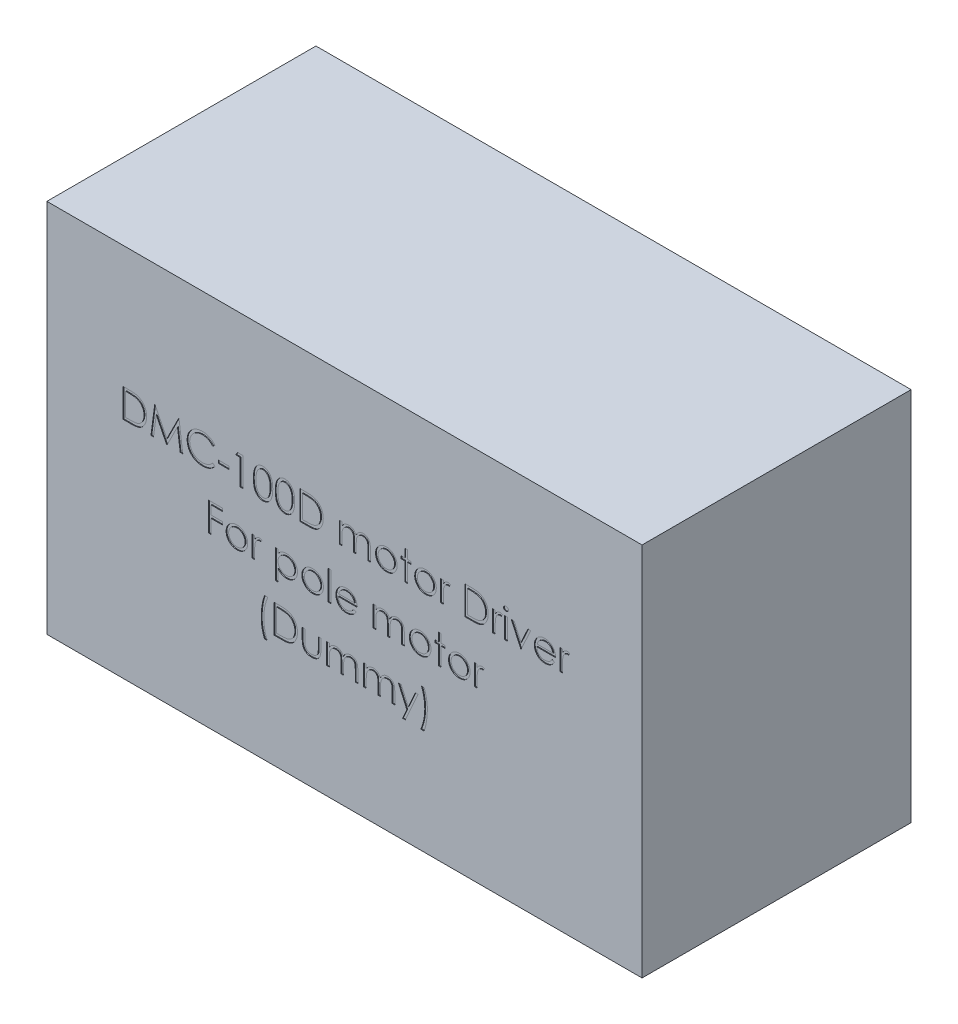
from build123d import *

# Parameters (mm, degrees)
SKETCH_1_W          = 73
SKETCH_1_H          = 46
EXTRUDE_1_DEPTH     = 33
SKETCH_2_W          = 1.346153846
SKETCH_2_H          = 0.358974359
SKETCH_2_W_2        = 0.314102564
SKETCH_2_H_2        = 2.557692308
SKETCH_2_H_3        = 3.589743589
CUT_EXTRUDE_1_DEPTH = 0.1


with BuildPart() as part:
    # 스케치1 → 보스-돌출1 (new body)
    with BuildSketch(Plane.XY):
        Rectangle(SKETCH_1_W, SKETCH_1_H)
    extrude(amount=EXTRUDE_1_DEPTH)

    # 스케치2 → 컷-돌출1 (cut)
    # profile 1 of 39: a face of its own
    with BuildSketch(Plane.XY.offset(33)):
        with BuildLine():
            Line((-27.147435897, 4.514894335), (-27.147435897, 8.014894335))
            Line((-27.147435897, 8.014894335), (-26.440705128, 8.014894335))
            add(Edge.make_bspline(
                [(-26.440705128, 8.014894335), (-26.37923614, 8.014451765), (-26.260478375, 8.013596722), (-26.088865927, 8.008175331), (-25.930082165, 7.998584865), (-25.784649306, 7.984615339), (-25.652168094, 7.967462305), (-25.533009486, 7.945961901), (-25.426557343, 7.920573731), (-25.361087902, 7.89892828), (-25.330128205, 7.888692412)],
                knots=[0, 0, 0, 0, 1.314313732, 2.53924729, 3.670748893, 4.714932338, 5.66265055, 6.526160246, 7.303039223, 8, 8, 8, 8], degree=3))
            add(Edge.make_bspline(
                [(-25.330128205, 7.888692412), (-25.289633466, 7.873261706), (-25.209562274, 7.842750212), (-25.095555151, 7.785193911), (-24.988229788, 7.719980809), (-24.887010643, 7.647024946), (-24.794209817, 7.564260598), (-24.70620192, 7.475203512), (-24.626587196, 7.376615172), (-24.5536789, 7.270540184), (-24.487943241, 7.158228132), (-24.430804083, 7.039893023), (-24.38335009, 6.916135815), (-24.343956863, 6.787300667), (-24.312910405, 6.653104289), (-24.291728474, 6.513390423), (-24.277757484, 6.368711234), (-24.276353432, 6.27053677), (-24.275641026, 6.220723662)],
                knots=[0, 0, 0, 0, 0.984719456, 1.947108742, 2.898477687, 3.838006223, 4.779231079, 5.722358779, 6.681677486, 7.655904652, 8.64651281, 9.637519902, 10.640069247, 11.656948941, 12.698408672, 13.768548281, 14.867775369, 16, 16, 16, 16], degree=3))
            add(Edge.make_bspline(
                [(-24.275641026, 6.220723662), (-24.276269993, 6.177462423), (-24.277509439, 6.092211634), (-24.288638755, 5.966570739), (-24.304815075, 5.844657167), (-24.329859273, 5.727051467), (-24.360261786, 5.61272325), (-24.399225938, 5.502891005), (-24.443861434, 5.396547196), (-24.495911312, 5.29512972), (-24.553052697, 5.199046348), (-24.614374441, 5.10847082), (-24.679811136, 5.024695598), (-24.749986769, 4.947466986), (-24.823994485, 4.876901407), (-24.902318816, 4.812409392), (-24.985161867, 4.755252837), (-25.07215259, 4.703185729), (-25.165828719, 4.657765373), (-25.267964585, 4.619335364), (-25.378995763, 4.587488748), (-25.49864972, 4.560917852), (-25.627133198, 4.53984055), (-25.764572163, 4.525714157), (-25.910755453, 4.516161225), (-26.011134718, 4.515324831), (-26.062800481, 4.514894335)],
                knots=[0, 0, 0, 0, 1.105936401, 2.179363191, 3.223086493, 4.248585256, 5.251745608, 6.245858792, 7.225916811, 8.198733463, 9.158002045, 10.082870192, 10.993790845, 11.873723703, 12.748670949, 13.606408763, 14.465103618, 15.319838547, 16.196477973, 17.123216899, 18.106603292, 19.147568657, 20.255746949, 21.433717677, 22.679120308, 24, 24, 24, 24], degree=3))
            Line((-26.062800481, 4.514894335), (-27.147435897, 4.514894335))
        make_face()
        with BuildLine():
            Line((-26.833333333, 4.873868694), (-26.431590545, 4.873868694))
            add(Edge.make_bspline(
                [(-26.431590545, 4.873868694), (-26.373862174, 4.87411679), (-26.262829376, 4.87459397), (-26.103171378, 4.878781174), (-25.957291982, 4.885623111), (-25.825170473, 4.895198189), (-25.706881448, 4.907866804), (-25.602177698, 4.921991707), (-25.51140244, 4.939589158), (-25.456473003, 4.955540117), (-25.431089744, 4.962911162)],
                knots=[0, 0, 0, 0, 1.375205317, 2.645023457, 3.804390687, 4.853969522, 5.800190428, 6.637939096, 7.370582563, 8, 8, 8, 8], degree=3))
            add(Edge.make_bspline(
                [(-25.431089744, 4.962911162), (-25.399141382, 4.97416272), (-25.336007743, 4.996397093), (-25.245126658, 5.036954755), (-25.160369653, 5.084996824), (-25.080259628, 5.138399098), (-25.005932973, 5.1990451), (-24.936508856, 5.265616089), (-24.872127055, 5.338450864), (-24.813452747, 5.417459026), (-24.760944443, 5.502148821), (-24.715473214, 5.591687655), (-24.675621682, 5.685094465), (-24.644343089, 5.783803624), (-24.619827505, 5.886932682), (-24.602462817, 5.994488896), (-24.591648093, 6.106452177), (-24.590386645, 6.182604302), (-24.58974359, 6.221424784)],
                knots=[0, 0, 0, 0, 0.998632004, 1.973411704, 2.929992603, 3.868527914, 4.809262121, 5.754881198, 6.702106254, 7.672490631, 8.653608572, 9.636854334, 10.631411391, 11.644891563, 12.686317036, 13.754757253, 14.855430412, 16, 16, 16, 16], degree=3))
            add(Edge.make_bspline(
                [(-24.58974359, 6.221424784), (-24.590256877, 6.262358264), (-24.591265235, 6.342772448), (-24.603939545, 6.460763144), (-24.622461101, 6.574243794), (-24.649244787, 6.68322199), (-24.683375665, 6.787910342), (-24.725970307, 6.887729852), (-24.774636927, 6.983734721), (-24.832540263, 7.073709086), (-24.895955857, 7.158802196), (-24.966333736, 7.236757111), (-25.042555775, 7.307751411), (-25.123790624, 7.372890724), (-25.212327723, 7.4295544), (-25.306081414, 7.480241081), (-25.406427085, 7.523256972), (-25.476239781, 7.546135835), (-25.51171875, 7.557762925)],
                knots=[0, 0, 0, 0, 1.122418816, 2.205001699, 3.251619955, 4.274784885, 5.280384055, 6.268708349, 7.249350384, 8.229342522, 9.199999885, 10.157847722, 11.105861043, 12.055065948, 13.010012805, 13.98527497, 14.976112212, 16, 16, 16, 16], degree=3))
            add(Edge.make_bspline(
                [(-25.51171875, 7.557762925), (-25.541069896, 7.565879353), (-25.603478487, 7.583137105), (-25.705317951, 7.601962478), (-25.8199331, 7.618566977), (-25.947832801, 7.632625016), (-26.08887126, 7.642712337), (-26.243156948, 7.650283652), (-26.410756553, 7.655390284), (-26.526939087, 7.655738992), (-26.587239583, 7.655919976)],
                knots=[0, 0, 0, 0, 0.674548936, 1.434276114, 2.292660221, 3.240891867, 4.284742987, 5.42552168, 6.663806718, 8, 8, 8, 8], degree=3))
            Line((-26.587239583, 7.655919976), (-26.833333333, 7.655919976))
            Line((-26.833333333, 7.655919976), (-26.833333333, 4.873868694))
        make_face(mode=Mode.SUBTRACT)
    # profile 2 of 39: a face of its own
    with BuildSketch(Plane.XY.offset(33)):
        Polygon((-23.737179487, 4.514894335), (-23.275140224, 8.014894335), (-23.230268429, 8.014894335), (-21.78525641, 5.143099463), (-20.34375, 8.014894335), (-20.298177083, 8.014894335), (-19.833333333, 4.514894335), (-20.148838141, 4.514894335), (-20.483974359, 7.033323822), (-21.747395833, 4.514894335), (-21.818209135, 4.514894335), (-23.086538462, 7.038932796), (-23.420973558, 4.514894335), align=None)
    # profile 3 of 39: a face of its own
    with BuildSketch(Plane.XY.offset(33)):
        with BuildLine():
            Line((-15.884615385, 7.372666771), (-16.159455128, 7.162330232))
            add(Edge.make_bspline(
                [(-16.159455128, 7.162330232), (-16.179061017, 7.185696202), (-16.218008463, 7.232113118), (-16.280667666, 7.297292662), (-16.345969309, 7.358357924), (-16.41388843, 7.415599803), (-16.48564755, 7.467016569), (-16.559508348, 7.515287672), (-16.636706393, 7.55855541), (-16.743458128, 7.611018396), (-16.883105976, 7.665764551), (-17.058900815, 7.711667783), (-17.242411914, 7.740888958), (-17.367609513, 7.7440538), (-17.431290064, 7.745663566)],
                knots=[0, 0, 0, 0, 0.757959112, 1.505699292, 2.245454638, 2.979532153, 3.711538275, 4.438200793, 5.171680507, 5.909471876, 7.393775596, 8.890124382, 10.418191784, 12, 12, 12, 12], degree=3))
            add(Edge.make_bspline(
                [(-17.431290064, 7.745663566), (-17.466373363, 7.745259603), (-17.536214356, 7.744455427), (-17.63986283, 7.733846302), (-17.741575881, 7.718935092), (-17.841287347, 7.696809769), (-17.938870305, 7.66883715), (-18.034962707, 7.635411736), (-18.128173307, 7.594056896), (-18.219791545, 7.548348636), (-18.307570756, 7.496721191), (-18.390625804, 7.440407839), (-18.468653772, 7.380038743), (-18.541716384, 7.315387637), (-18.609888333, 7.246745676), (-18.672675643, 7.173381335), (-18.729861054, 7.095529161), (-18.782578079, 7.014215753), (-18.829790812, 6.929677962), (-18.869320692, 6.841602891), (-18.904325814, 6.751498788), (-18.932025056, 6.658347628), (-18.953949573, 6.562804862), (-18.969077236, 6.464614074), (-18.979565708, 6.363980394), (-18.980365885, 6.295771082), (-18.980769231, 6.261388726)],
                knots=[0, 0, 0, 0, 1.054917814, 2.100044995, 3.131103042, 4.146048494, 5.169673617, 6.183595914, 7.203665975, 8.234915748, 9.262203917, 10.264457458, 11.251630812, 12.227803204, 13.197192746, 14.159520551, 15.12972552, 16.100847026, 17.073214652, 18.039054194, 19.002613845, 19.979014051, 20.95965708, 21.949030935, 22.966165397, 24, 24, 24, 24], degree=3))
            add(Edge.make_bspline(
                [(-18.980769231, 6.261388726), (-18.979507412, 6.209657406), (-18.977029997, 6.108089821), (-18.954981663, 5.959319211), (-18.921476572, 5.816798537), (-18.871260995, 5.681418695), (-18.809341945, 5.551510337), (-18.731101333, 5.429271483), (-18.640484796, 5.312854919), (-18.536210376, 5.205011971), (-18.42180456, 5.106498246), (-18.299056649, 5.019747664), (-18.168272361, 4.947432782), (-18.030895731, 4.887256835), (-17.885869617, 4.841000107), (-17.733454814, 4.808435984), (-17.573982819, 4.787193803), (-17.465013419, 4.785160115), (-17.409555288, 4.784125104)],
                knots=[0, 0, 0, 0, 1.029171465, 2.020641659, 2.987623507, 3.938342917, 4.889210282, 5.84687017, 6.821220943, 7.821438502, 8.827599549, 9.822697543, 10.807740252, 11.797342354, 12.80366471, 13.83203677, 14.896651826, 16, 16, 16, 16], degree=3))
            add(Edge.make_bspline(
                [(-17.409555288, 4.784125104), (-17.348452599, 4.785813884), (-17.228187891, 4.789137806), (-17.051819864, 4.817297056), (-16.882984099, 4.862954973), (-16.721671512, 4.926852896), (-16.568336866, 5.009918184), (-16.422740206, 5.110616061), (-16.284758635, 5.229904394), (-16.201787353, 5.320987522), (-16.159455128, 5.367458438)],
                knots=[0, 0, 0, 0, 1.028121516, 2.023589091, 2.998037872, 3.967518031, 4.937445131, 5.927275754, 6.942489185, 8, 8, 8, 8], degree=3))
            Line((-16.159455128, 5.367458438), (-15.884615385, 5.159225264))
            add(Edge.make_bspline(
                [(-15.884615385, 5.159225264), (-15.906733494, 5.130686813), (-15.95086377, 5.073746606), (-16.022321787, 4.993474897), (-16.097599084, 4.917970861), (-16.177254794, 4.84784324), (-16.260372586, 4.781688774), (-16.348444898, 4.721386943), (-16.440313931, 4.666096059), (-16.535668409, 4.615469134), (-16.634407022, 4.570551887), (-16.736411457, 4.532098119), (-16.841242033, 4.49897323), (-16.948903541, 4.471721293), (-17.059619298, 4.450450209), (-17.172989772, 4.436230534), (-17.289259647, 4.42648862), (-17.367701068, 4.425600704), (-17.407451923, 4.425150745)],
                knots=[0, 0, 0, 0, 0.986787822, 1.968848986, 2.935600012, 3.899624008, 4.868462664, 5.837806735, 6.815139263, 7.798259679, 8.787526145, 9.778297419, 10.776456485, 11.791383307, 12.812564526, 13.85620153, 14.913611965, 16, 16, 16, 16], degree=3))
            add(Edge.make_bspline(
                [(-17.407451923, 4.425150745), (-17.44509559, 4.425412738), (-17.51953128, 4.425930796), (-17.629430032, 4.434322963), (-17.736419613, 4.4457727), (-17.840194239, 4.463012831), (-17.941320214, 4.483357171), (-18.038880798, 4.510628428), (-18.133836008, 4.541177594), (-18.225804349, 4.577082581), (-18.314864049, 4.617598764), (-18.40072786, 4.663390322), (-18.483356293, 4.714072187), (-18.563561714, 4.768527198), (-18.640159297, 4.828504499), (-18.713812823, 4.893171134), (-18.784935299, 4.962309145), (-18.828937984, 5.012163998), (-18.851061699, 5.037230072)],
                knots=[0, 0, 0, 0, 1.114604814, 2.203992996, 3.262667896, 4.300477797, 5.318619304, 6.316056647, 7.298880507, 8.271930387, 9.238335007, 10.195173496, 11.151986948, 12.108099108, 13.064862484, 14.031167946, 15.010108607, 16, 16, 16, 16], degree=3))
            add(Edge.make_bspline(
                [(-18.851061699, 5.037230072), (-18.886497342, 5.080771261), (-18.956940819, 5.167327971), (-19.047066503, 5.307613953), (-19.124214058, 5.454082162), (-19.186589979, 5.60750209), (-19.235352712, 5.767529478), (-19.269133907, 5.934244992), (-19.291085511, 6.107492934), (-19.2935958, 6.225329723), (-19.294871795, 6.285226867)],
                knots=[0, 0, 0, 0, 0.994628077, 1.977248131, 2.950237994, 3.925870899, 4.908910175, 5.911660606, 6.938484602, 8, 8, 8, 8], degree=3))
            add(Edge.make_bspline(
                [(-19.294871795, 6.285226867), (-19.293316601, 6.348182321), (-19.290256855, 6.472043245), (-19.26426106, 6.653817198), (-19.222442263, 6.827968597), (-19.163045375, 6.994172342), (-19.087740024, 7.153302622), (-18.99471341, 7.304143827), (-18.885046267, 7.447660627), (-18.7595987, 7.581675378), (-18.622031364, 7.70421473), (-18.474712551, 7.812020934), (-18.317930604, 7.90173845), (-18.153412752, 7.976734613), (-17.97992707, 8.034379076), (-17.797843701, 8.074732262), (-17.607504786, 8.099849379), (-17.477642361, 8.103024587), (-17.411658654, 8.104637925)],
                knots=[0, 0, 0, 0, 1.032925535, 2.032216505, 3.007276963, 3.968222605, 4.92396291, 5.891752235, 6.871517503, 7.883894988, 8.900124299, 9.891468569, 10.874487609, 11.85992873, 12.854644235, 13.869047385, 14.917252991, 16, 16, 16, 16], degree=3))
            add(Edge.make_bspline(
                [(-17.411658654, 8.104637925), (-17.371444182, 8.104155786), (-17.291843685, 8.103201442), (-17.174091032, 8.0938953), (-17.059448705, 8.078381694), (-16.947837723, 8.057265624), (-16.838715107, 8.031058303), (-16.732914866, 7.996918005), (-16.629816179, 7.957881473), (-16.530069271, 7.912923007), (-16.434152721, 7.862456266), (-16.342096402, 7.807040642), (-16.254631544, 7.746744837), (-16.171142695, 7.682081661), (-16.093026484, 7.611683102), (-16.018065006, 7.537485506), (-15.948803928, 7.457351682), (-15.906050733, 7.400946748), (-15.884615385, 7.372666771)],
                knots=[0, 0, 0, 0, 1.096760587, 2.17092713, 3.219439832, 4.250915756, 5.268269357, 6.278326846, 7.281116186, 8.274029601, 9.260640565, 10.235837813, 11.203064059, 12.156899882, 13.114053108, 14.069676657, 15.032185724, 16, 16, 16, 16], degree=3))
        make_face()
    # profile 4 of 39: a face of its own
    with BuildSketch(Plane.XY.offset(33)):
        with Locations((-14.807692308, 5.861048182)):
            Rectangle(SKETCH_2_W, SKETCH_2_H)
    # profile 5 of 39: a face of its own
    with BuildSketch(Plane.XY.offset(33)):
        Polygon((-13.121494391, 8.014894335), (-12.474358974, 8.014894335), (-12.474358974, 4.514894335), (-12.788461538, 4.514894335), (-12.788461538, 7.655919976), (-13.326923077, 7.655919976), align=None)
    # profile 6 of 39: a face of its own
    with BuildSketch(Plane.XY.offset(33)):
        with BuildLine():
            add(Edge.make_bspline(
                [(-11.173076923, 6.263492091), (-11.172748905, 6.319589479), (-11.172111725, 6.428559463), (-11.165023304, 6.587344105), (-11.153247962, 6.736304394), (-11.137110589, 6.87544746), (-11.117472609, 7.004809225), (-11.091257122, 7.124043982), (-11.061444319, 7.233703589), (-11.026891874, 7.334145637), (-10.987904085, 7.42672334), (-10.945469824, 7.513148541), (-10.897905029, 7.593290474), (-10.847928116, 7.668428264), (-10.793516045, 7.737331959), (-10.736217254, 7.800974622), (-10.673795378, 7.857885372), (-10.60837237, 7.909731674), (-10.539355905, 7.955181146), (-10.468713239, 7.995213885), (-10.395958133, 8.029413752), (-10.320891951, 8.056304188), (-10.244189393, 8.078515035), (-10.165582326, 8.093703982), (-10.084940962, 8.103260891), (-10.030509527, 8.104174558), (-10.002904647, 8.104637925)],
                knots=[0, 0, 0, 0, 1.646270934, 3.197905019, 4.663502075, 6.030701355, 7.308322542, 8.50163776, 9.611534131, 10.641858119, 11.616356847, 12.558055219, 13.465016945, 14.349605745, 15.204443733, 16.039544428, 16.859896111, 17.680448484, 18.487036065, 19.28249412, 20.06191084, 20.843045899, 21.620316918, 22.403196591, 23.190181807, 24, 24, 24, 24], degree=3))
            add(Edge.make_bspline(
                [(-10.002904647, 8.104637925), (-9.975069169, 8.10415011), (-9.91971316, 8.103179999), (-9.837872785, 8.093856056), (-9.757923103, 8.078384933), (-9.680204964, 8.056463958), (-9.604079978, 8.029268282), (-9.53014357, 7.995181165), (-9.457936489, 7.955502297), (-9.388606201, 7.90887842), (-9.321391586, 7.856896144), (-9.257943623, 7.798133475), (-9.198256537, 7.733183756), (-9.141581232, 7.662741892), (-9.089525634, 7.585456807), (-9.039952202, 7.502672697), (-8.995580166, 7.412941832), (-8.952845491, 7.317761365), (-8.915958504, 7.214497706), (-8.882692259, 7.103732945), (-8.85581329, 6.984158758), (-8.833424018, 6.856402513), (-8.816079122, 6.71999503), (-8.80344648, 6.575228714), (-8.796773395, 6.422008324), (-8.795516694, 6.317250474), (-8.794871795, 6.263492091)],
                knots=[0, 0, 0, 0, 0.810914788, 1.612654377, 2.396697861, 3.181598691, 3.963628158, 4.749916497, 5.551656086, 6.361998678, 7.18212741, 8.025565596, 8.878627764, 9.750805457, 10.657531673, 11.591944965, 12.560506719, 13.57287815, 14.630710178, 15.753379473, 16.941251878, 18.199788006, 19.531962791, 20.947069417, 22.433333509, 24, 24, 24, 24], degree=3))
            add(Edge.make_bspline(
                [(-8.794871795, 6.263492091), (-8.795523379, 6.209968183), (-8.796792965, 6.105679032), (-8.803371672, 5.953148056), (-8.816330303, 5.809150013), (-8.832540292, 5.67333955), (-8.854991255, 5.546281932), (-8.882596421, 5.427537483), (-8.913246744, 5.316593412), (-8.951081538, 5.2143586), (-8.992492248, 5.119406877), (-9.037547444, 5.030739729), (-9.08581727, 4.947573436), (-9.138406015, 4.870573689), (-9.194459429, 4.799195032), (-9.255177217, 4.734697409), (-9.318847802, 4.675526737), (-9.386260218, 4.62287511), (-9.45667177, 4.576790305), (-9.528630846, 4.535576455), (-9.60341423, 4.50234376), (-9.679327183, 4.473808719), (-9.757455549, 4.452008267), (-9.837701939, 4.436934411), (-9.919658175, 4.426362563), (-9.97505974, 4.425556083), (-10.002904647, 4.425150745)],
                knots=[0, 0, 0, 0, 1.561518951, 3.042555995, 4.452378317, 5.7783523, 7.031515105, 8.214008947, 9.334062868, 10.386615937, 11.391082383, 12.354592575, 13.286541444, 14.194233754, 15.072674879, 15.931287219, 16.775624067, 17.606195743, 18.42308326, 19.229000347, 20.022332153, 20.807536673, 21.593273796, 22.3848459, 23.188221202, 24, 24, 24, 24], degree=3))
            add(Edge.make_bspline(
                [(-10.002904647, 4.425150745), (-10.030508761, 4.425617101), (-10.084938686, 4.426536663), (-10.165591112, 4.436050394), (-10.243873555, 4.451345897), (-10.320172309, 4.472762501), (-10.394878824, 4.498977338), (-10.466975111, 4.533131021), (-10.537262795, 4.57246509), (-10.605554351, 4.617260512), (-10.670566512, 4.668582195), (-10.732665117, 4.725346484), (-10.790290136, 4.788969895), (-10.843924232, 4.858447818), (-10.89489832, 4.93314106), (-10.941787693, 5.014069433), (-10.985158547, 5.100912044), (-11.024802038, 5.194229954), (-11.059950701, 5.295384882), (-11.090998409, 5.405534061), (-11.115512567, 5.525649697), (-11.136495522, 5.654767064), (-11.153419905, 5.793440994), (-11.164974231, 5.941746773), (-11.172115546, 6.099591982), (-11.172750616, 6.207861756), (-11.173076923, 6.263492091)],
                knots=[0, 0, 0, 0, 0.810891512, 1.598919785, 2.382837074, 3.152667961, 3.926044502, 4.706494248, 5.493654104, 6.291793342, 7.103789334, 7.925228297, 8.761435821, 9.622817696, 10.50288917, 11.416980706, 12.369136599, 13.353924996, 14.394355917, 15.514179734, 16.714354668, 17.994756427, 19.357759367, 20.818452758, 22.365282078, 24, 24, 24, 24], degree=3))
        make_face()
        with BuildLine():
            add(Edge.make_bspline(
                [(-10.858974359, 6.264894335), (-10.858854912, 6.218145636), (-10.858623089, 6.127415591), (-10.852566888, 5.99557233), (-10.844316656, 5.872602002), (-10.833675359, 5.758348465), (-10.81787241, 5.653198453), (-10.800165622, 5.55642877), (-10.778617533, 5.468551532), (-10.753122515, 5.388963722), (-10.724083418, 5.316314653), (-10.692377554, 5.248713438), (-10.658316832, 5.185361502), (-10.620197681, 5.126827893), (-10.578682618, 5.072921729), (-10.534709359, 5.022688897), (-10.486636774, 4.977891916), (-10.420133032, 4.92416506), (-10.332336557, 4.868645927), (-10.221716102, 4.820299837), (-10.108047651, 4.78991738), (-10.030896401, 4.786053625), (-9.992387821, 4.784125104)],
                knots=[0, 0, 0, 0, 1.459021318, 2.831673884, 4.118529203, 5.306027144, 6.411944654, 7.436330062, 8.375795394, 9.233974572, 10.042671642, 10.816086306, 11.563610507, 12.285937304, 12.993564865, 13.685989202, 14.367179055, 15.041617293, 16.353048772, 17.594441528, 18.799311195, 20, 20, 20, 20], degree=3))
            add(Edge.make_bspline(
                [(-9.992387821, 4.784125104), (-9.953630149, 4.785722885), (-9.876194826, 4.788915148), (-9.763061031, 4.819713885), (-9.65323076, 4.866183425), (-9.56715882, 4.92113093), (-9.501676277, 4.973459259), (-9.454759287, 5.018073908), (-9.411697238, 5.068029775), (-9.370855163, 5.121929071), (-9.333396088, 5.180801555), (-9.29933295, 5.24436413), (-9.268249602, 5.312793308), (-9.250540556, 5.360563047), (-9.241486378, 5.384986482)],
                knots=[0, 0, 0, 0, 1.353760809, 2.704726607, 4.075137775, 5.516104923, 6.260822281, 7.007110065, 7.778089737, 8.566572457, 9.372053459, 10.217411131, 11.088608312, 12, 12, 12, 12], degree=3))
            add(Edge.make_bspline(
                [(-9.241486378, 5.384986482), (-9.23093461, 5.416216222), (-9.209509997, 5.479625986), (-9.181898222, 5.577989638), (-9.160152823, 5.681192402), (-9.140589457, 5.788617519), (-9.127236401, 5.90105722), (-9.116488588, 6.018163604), (-9.110157901, 6.140024966), (-9.10937315, 6.222819957), (-9.108974359, 6.264894335)],
                knots=[0, 0, 0, 0, 0.884706709, 1.796334032, 2.740027952, 3.714592787, 4.726048262, 5.777819803, 6.87074269, 8, 8, 8, 8], degree=3))
            add(Edge.make_bspline(
                [(-9.108974359, 6.264894335), (-9.109524548, 6.306961907), (-9.110600836, 6.389255072), (-9.114714824, 6.509773253), (-9.125338398, 6.624241014), (-9.137137517, 6.733151486), (-9.154534738, 6.835901789), (-9.173292545, 6.933352094), (-9.198493757, 7.024295119), (-9.225413532, 7.110154701), (-9.256223928, 7.189955355), (-9.290139662, 7.264069142), (-9.326361421, 7.332853867), (-9.365703661, 7.396120808), (-9.407699344, 7.454153351), (-9.453456894, 7.505787946), (-9.501161266, 7.552624914), (-9.567978452, 7.606087483), (-9.655452742, 7.660599178), (-9.764298389, 7.710764938), (-9.877569034, 7.739573231), (-9.954142488, 7.743634918), (-9.992387821, 7.745663566)],
                knots=[0, 0, 0, 0, 1.31362396, 2.569729283, 3.763502607, 4.902122613, 5.988968491, 7.01645872, 7.998833611, 8.933434873, 9.825090667, 10.667526885, 11.477055099, 12.250526234, 12.991942729, 13.710640831, 14.402115721, 15.076753259, 16.378508321, 17.609869233, 18.806226677, 20, 20, 20, 20], degree=3))
            add(Edge.make_bspline(
                [(-9.992387821, 7.745663566), (-10.031098413, 7.743632119), (-10.108590118, 7.739565525), (-10.223038073, 7.710872271), (-10.332742425, 7.660859305), (-10.419985399, 7.605906933), (-10.486849186, 7.553568622), (-10.533931879, 7.508182167), (-10.578078051, 7.458535913), (-10.618745751, 7.404133998), (-10.656835035, 7.345668631), (-10.691816047, 7.282679866), (-10.723333377, 7.214848502), (-10.752417913, 7.142232067), (-10.777990701, 7.062651122), (-10.799084664, 6.974882129), (-10.818571717, 6.878420237), (-10.832366986, 6.772700729), (-10.844630742, 6.658418575), (-10.85251209, 6.535141257), (-10.858643348, 6.403076877), (-10.858861812, 6.311877718), (-10.858974359, 6.264894335)],
                knots=[0, 0, 0, 0, 1.207732386, 2.417664972, 3.655092373, 4.956220595, 5.625982001, 6.301752483, 6.994047911, 7.697131622, 8.419323945, 9.170223765, 9.943494443, 10.752040957, 11.610060368, 12.549350801, 13.567764191, 14.679664412, 15.874934091, 17.154273443, 18.533957287, 20, 20, 20, 20], degree=3))
        make_face(mode=Mode.SUBTRACT)
    # profile 7 of 39: a face of its own
    with BuildSketch(Plane.XY.offset(33)):
        with BuildLine():
            add(Edge.make_bspline(
                [(-8.480769231, 6.263492091), (-8.480441213, 6.319589479), (-8.479804033, 6.428559463), (-8.472715612, 6.587344105), (-8.460940269, 6.736304394), (-8.444802897, 6.87544746), (-8.425164916, 7.004809225), (-8.39894943, 7.124043982), (-8.369136627, 7.233703589), (-8.334584181, 7.334145637), (-8.295596392, 7.42672334), (-8.253162132, 7.513148541), (-8.205597337, 7.593290474), (-8.155620424, 7.668428264), (-8.101208353, 7.737331959), (-8.043909562, 7.800974622), (-7.981487686, 7.857885372), (-7.916064678, 7.909731674), (-7.847048213, 7.955181146), (-7.776405547, 7.995213885), (-7.703650441, 8.029413752), (-7.628584258, 8.056304188), (-7.5518817, 8.078515035), (-7.473274634, 8.093703982), (-7.39263327, 8.103260891), (-7.338201835, 8.104174558), (-7.310596955, 8.104637925)],
                knots=[0, 0, 0, 0, 1.646270934, 3.197905019, 4.663502075, 6.030701355, 7.308322542, 8.50163776, 9.611534131, 10.641858119, 11.616356847, 12.558055219, 13.465016945, 14.349605745, 15.204443733, 16.039544428, 16.859896111, 17.680448484, 18.487036065, 19.28249412, 20.06191084, 20.843045899, 21.620316918, 22.403196591, 23.190181807, 24, 24, 24, 24], degree=3))
            add(Edge.make_bspline(
                [(-7.310596955, 8.104637925), (-7.282761477, 8.10415011), (-7.227405468, 8.103179999), (-7.145565093, 8.093856056), (-7.065615411, 8.078384933), (-6.987897272, 8.056463958), (-6.911772286, 8.029268282), (-6.837835878, 7.995181165), (-6.765628796, 7.955502297), (-6.696298509, 7.90887842), (-6.629083893, 7.856896144), (-6.56563593, 7.798133475), (-6.505948845, 7.733183756), (-6.449273539, 7.662741892), (-6.397217942, 7.585456807), (-6.34764451, 7.502672697), (-6.303272474, 7.412941832), (-6.260537799, 7.317761365), (-6.223650812, 7.214497706), (-6.190384567, 7.103732945), (-6.163505598, 6.984158758), (-6.141116326, 6.856402513), (-6.12377143, 6.71999503), (-6.111138788, 6.575228714), (-6.104465703, 6.422008324), (-6.103209001, 6.317250474), (-6.102564103, 6.263492091)],
                knots=[0, 0, 0, 0, 0.810914788, 1.612654377, 2.396697861, 3.181598691, 3.963628158, 4.749916497, 5.551656086, 6.361998678, 7.18212741, 8.025565596, 8.878627764, 9.750805457, 10.657531673, 11.591944965, 12.560506719, 13.57287815, 14.630710178, 15.753379473, 16.941251878, 18.199788006, 19.531962791, 20.947069417, 22.433333509, 24, 24, 24, 24], degree=3))
            add(Edge.make_bspline(
                [(-6.102564103, 6.263492091), (-6.103215687, 6.209968183), (-6.104485273, 6.105679032), (-6.11106398, 5.953148056), (-6.124022611, 5.809150013), (-6.140232599, 5.67333955), (-6.162683562, 5.546281932), (-6.190288728, 5.427537483), (-6.220939051, 5.316593412), (-6.258773845, 5.2143586), (-6.300184556, 5.119406877), (-6.345239752, 5.030739729), (-6.393509578, 4.947573436), (-6.446098323, 4.870573689), (-6.502151736, 4.799195032), (-6.562869525, 4.734697409), (-6.62654011, 4.675526737), (-6.693952526, 4.62287511), (-6.764364077, 4.576790305), (-6.836323154, 4.535576455), (-6.911106537, 4.50234376), (-6.98701949, 4.473808719), (-7.065147856, 4.452008267), (-7.145394247, 4.436934411), (-7.227350483, 4.426362563), (-7.282752048, 4.425556083), (-7.310596955, 4.425150745)],
                knots=[0, 0, 0, 0, 1.561518951, 3.042555995, 4.452378317, 5.7783523, 7.031515105, 8.214008947, 9.334062868, 10.386615937, 11.391082383, 12.354592575, 13.286541444, 14.194233754, 15.072674879, 15.931287219, 16.775624067, 17.606195743, 18.42308326, 19.229000347, 20.022332153, 20.807536673, 21.593273796, 22.3848459, 23.188221202, 24, 24, 24, 24], degree=3))
            add(Edge.make_bspline(
                [(-7.310596955, 4.425150745), (-7.338201069, 4.425617101), (-7.392630994, 4.426536663), (-7.473283419, 4.436050394), (-7.551565863, 4.451345897), (-7.627864617, 4.472762501), (-7.702571132, 4.498977338), (-7.774667419, 4.533131021), (-7.844955102, 4.57246509), (-7.913246658, 4.617260512), (-7.978258819, 4.668582195), (-8.040357425, 4.725346484), (-8.097982444, 4.788969895), (-8.151616539, 4.858447818), (-8.202590628, 4.93314106), (-8.249480001, 5.014069433), (-8.292850855, 5.100912044), (-8.332494346, 5.194229954), (-8.367643009, 5.295384882), (-8.398690717, 5.405534061), (-8.423204875, 5.525649697), (-8.44418783, 5.654767064), (-8.461112213, 5.793440994), (-8.472666538, 5.941746773), (-8.479807853, 6.099591982), (-8.480442924, 6.207861756), (-8.480769231, 6.263492091)],
                knots=[0, 0, 0, 0, 0.810891512, 1.598919785, 2.382837074, 3.152667961, 3.926044502, 4.706494248, 5.493654104, 6.291793342, 7.103789334, 7.925228297, 8.761435821, 9.622817696, 10.50288917, 11.416980706, 12.369136599, 13.353924996, 14.394355917, 15.514179734, 16.714354668, 17.994756427, 19.357759367, 20.818452758, 22.365282078, 24, 24, 24, 24], degree=3))
        make_face()
        with BuildLine():
            add(Edge.make_bspline(
                [(-8.166666667, 6.264894335), (-8.16654722, 6.218145636), (-8.166315396, 6.127415591), (-8.160259196, 5.99557233), (-8.152008964, 5.872602002), (-8.141367667, 5.758348465), (-8.125564718, 5.653198453), (-8.10785793, 5.55642877), (-8.086309841, 5.468551532), (-8.060814823, 5.388963722), (-8.031775726, 5.316314653), (-8.000069862, 5.248713438), (-7.966009139, 5.185361502), (-7.927889989, 5.126827893), (-7.886374925, 5.072921729), (-7.842401666, 5.022688897), (-7.794329082, 4.977891916), (-7.72782534, 4.92416506), (-7.640028865, 4.868645927), (-7.52940841, 4.820299837), (-7.415739959, 4.78991738), (-7.338588709, 4.786053625), (-7.300080128, 4.784125104)],
                knots=[0, 0, 0, 0, 1.459021318, 2.831673884, 4.118529203, 5.306027144, 6.411944654, 7.436330062, 8.375795394, 9.233974572, 10.042671642, 10.816086306, 11.563610507, 12.285937304, 12.993564865, 13.685989202, 14.367179055, 15.041617293, 16.353048772, 17.594441528, 18.799311195, 20, 20, 20, 20], degree=3))
            add(Edge.make_bspline(
                [(-7.300080128, 4.784125104), (-7.261322457, 4.785722885), (-7.183887133, 4.788915148), (-7.070753338, 4.819713885), (-6.960923068, 4.866183425), (-6.874851128, 4.92113093), (-6.809368584, 4.973459259), (-6.762451594, 5.018073908), (-6.719389546, 5.068029775), (-6.678547471, 5.121929071), (-6.641088395, 5.180801555), (-6.607025258, 5.24436413), (-6.57594191, 5.312793308), (-6.558232864, 5.360563047), (-6.549178686, 5.384986482)],
                knots=[0, 0, 0, 0, 1.353760809, 2.704726607, 4.075137775, 5.516104923, 6.260822281, 7.007110065, 7.778089737, 8.566572457, 9.372053459, 10.217411131, 11.088608312, 12, 12, 12, 12], degree=3))
            add(Edge.make_bspline(
                [(-6.549178686, 5.384986482), (-6.538626918, 5.416216222), (-6.517202304, 5.479625986), (-6.48959053, 5.577989638), (-6.467845131, 5.681192402), (-6.448281765, 5.788617519), (-6.434928709, 5.90105722), (-6.424180896, 6.018163604), (-6.417850209, 6.140024966), (-6.417065458, 6.222819957), (-6.416666667, 6.264894335)],
                knots=[0, 0, 0, 0, 0.884706709, 1.796334032, 2.740027952, 3.714592787, 4.726048262, 5.777819803, 6.87074269, 8, 8, 8, 8], degree=3))
            add(Edge.make_bspline(
                [(-6.416666667, 6.264894335), (-6.417216856, 6.306961907), (-6.418293144, 6.389255072), (-6.422407131, 6.509773253), (-6.433030706, 6.624241014), (-6.444829825, 6.733151486), (-6.462227046, 6.835901789), (-6.480984853, 6.933352094), (-6.506186065, 7.024295119), (-6.53310584, 7.110154701), (-6.563916235, 7.189955355), (-6.59783197, 7.264069142), (-6.634053729, 7.332853867), (-6.673395969, 7.396120808), (-6.715391652, 7.454153351), (-6.761149201, 7.505787946), (-6.808853574, 7.552624914), (-6.87567076, 7.606087483), (-6.96314505, 7.660599178), (-7.071990697, 7.710764938), (-7.185261341, 7.739573231), (-7.261834795, 7.743634918), (-7.300080128, 7.745663566)],
                knots=[0, 0, 0, 0, 1.31362396, 2.569729283, 3.763502607, 4.902122613, 5.988968491, 7.01645872, 7.998833611, 8.933434873, 9.825090667, 10.667526885, 11.477055099, 12.250526234, 12.991942729, 13.710640831, 14.402115721, 15.076753259, 16.378508321, 17.609869233, 18.806226677, 20, 20, 20, 20], degree=3))
            add(Edge.make_bspline(
                [(-7.300080128, 7.745663566), (-7.33879072, 7.743632119), (-7.416282426, 7.739565525), (-7.530730381, 7.710872271), (-7.640434732, 7.660859305), (-7.727677707, 7.605906933), (-7.794541493, 7.553568622), (-7.841624187, 7.508182167), (-7.885770359, 7.458535913), (-7.926438059, 7.404133998), (-7.964527342, 7.345668631), (-7.999508355, 7.282679866), (-8.031025685, 7.214848502), (-8.060110221, 7.142232067), (-8.085683009, 7.062651122), (-8.106776972, 6.974882129), (-8.126264025, 6.878420237), (-8.140059294, 6.772700729), (-8.15232305, 6.658418575), (-8.160204398, 6.535141257), (-8.166335655, 6.403076877), (-8.16655412, 6.311877718), (-8.166666667, 6.264894335)],
                knots=[0, 0, 0, 0, 1.207732386, 2.417664972, 3.655092373, 4.956220595, 5.625982001, 6.301752483, 6.994047911, 7.697131622, 8.419323945, 9.170223765, 9.943494443, 10.752040957, 11.610060368, 12.549350801, 13.567764191, 14.679664412, 15.874934091, 17.154273443, 18.533957287, 20, 20, 20, 20], degree=3))
        make_face(mode=Mode.SUBTRACT)
    # profile 8 of 39: a face of its own
    with BuildSketch(Plane.XY.offset(33)):
        with BuildLine():
            Line((-5.474358974, 4.514894335), (-5.474358974, 8.014894335))
            Line((-5.474358974, 8.014894335), (-4.767628205, 8.014894335))
            add(Edge.make_bspline(
                [(-4.767628205, 8.014894335), (-4.706159217, 8.014451765), (-4.587401452, 8.013596722), (-4.415789004, 8.008175331), (-4.257005242, 7.998584865), (-4.111572383, 7.984615339), (-3.979091171, 7.967462305), (-3.859932563, 7.945961901), (-3.75348042, 7.920573731), (-3.688010979, 7.89892828), (-3.657051282, 7.888692412)],
                knots=[0, 0, 0, 0, 1.314313732, 2.53924729, 3.670748893, 4.714932338, 5.66265055, 6.526160246, 7.303039223, 8, 8, 8, 8], degree=3))
            add(Edge.make_bspline(
                [(-3.657051282, 7.888692412), (-3.616556543, 7.873261706), (-3.53648535, 7.842750212), (-3.422478228, 7.785193911), (-3.315152865, 7.719980809), (-3.21393372, 7.647024946), (-3.121132894, 7.564260598), (-3.033124997, 7.475203512), (-2.953510273, 7.376615172), (-2.880601977, 7.270540184), (-2.814866318, 7.158228132), (-2.75772716, 7.039893023), (-2.710273166, 6.916135815), (-2.67087994, 6.787300667), (-2.639833482, 6.653104289), (-2.618651551, 6.513390423), (-2.604680561, 6.368711234), (-2.603276509, 6.27053677), (-2.602564103, 6.220723662)],
                knots=[0, 0, 0, 0, 0.984719456, 1.947108742, 2.898477687, 3.838006223, 4.779231079, 5.722358779, 6.681677486, 7.655904652, 8.64651281, 9.637519902, 10.640069247, 11.656948941, 12.698408672, 13.768548281, 14.867775369, 16, 16, 16, 16], degree=3))
            add(Edge.make_bspline(
                [(-2.602564103, 6.220723662), (-2.60319307, 6.177462423), (-2.604432516, 6.092211634), (-2.615561832, 5.966570739), (-2.631738152, 5.844657167), (-2.65678235, 5.727051467), (-2.687184863, 5.61272325), (-2.726149015, 5.502891005), (-2.770784511, 5.396547196), (-2.822834389, 5.29512972), (-2.879975774, 5.199046348), (-2.941297518, 5.10847082), (-3.006734213, 5.024695598), (-3.076909846, 4.947466986), (-3.150917562, 4.876901407), (-3.229241893, 4.812409392), (-3.312084944, 4.755252837), (-3.399075666, 4.703185729), (-3.492751796, 4.657765373), (-3.594887662, 4.619335364), (-3.70591884, 4.587488748), (-3.825572797, 4.560917852), (-3.954056274, 4.53984055), (-4.09149524, 4.525714157), (-4.23767853, 4.516161225), (-4.338057795, 4.515324831), (-4.389723558, 4.514894335)],
                knots=[0, 0, 0, 0, 1.105936401, 2.179363191, 3.223086493, 4.248585256, 5.251745608, 6.245858792, 7.225916811, 8.198733463, 9.158002045, 10.082870192, 10.993790845, 11.873723703, 12.748670949, 13.606408763, 14.465103618, 15.319838547, 16.196477973, 17.123216899, 18.106603292, 19.147568657, 20.255746949, 21.433717677, 22.679120308, 24, 24, 24, 24], degree=3))
            Line((-4.389723558, 4.514894335), (-5.474358974, 4.514894335))
        make_face()
        with BuildLine():
            Line((-5.16025641, 4.873868694), (-4.758513622, 4.873868694))
            add(Edge.make_bspline(
                [(-4.758513622, 4.873868694), (-4.700785251, 4.87411679), (-4.589752453, 4.87459397), (-4.430094455, 4.878781174), (-4.284215059, 4.885623111), (-4.152093549, 4.895198189), (-4.033804525, 4.907866804), (-3.929100775, 4.921991707), (-3.838325517, 4.939589158), (-3.78339608, 4.955540117), (-3.758012821, 4.962911162)],
                knots=[0, 0, 0, 0, 1.375205317, 2.645023457, 3.804390687, 4.853969522, 5.800190428, 6.637939096, 7.370582563, 8, 8, 8, 8], degree=3))
            add(Edge.make_bspline(
                [(-3.758012821, 4.962911162), (-3.726064458, 4.97416272), (-3.66293082, 4.996397093), (-3.572049735, 5.036954755), (-3.48729273, 5.084996824), (-3.407182705, 5.138399098), (-3.33285605, 5.1990451), (-3.263431933, 5.265616089), (-3.199050132, 5.338450864), (-3.140375824, 5.417459026), (-3.08786752, 5.502148821), (-3.042396291, 5.591687655), (-3.002544759, 5.685094465), (-2.971266166, 5.783803624), (-2.946750582, 5.886932682), (-2.929385894, 5.994488896), (-2.91857117, 6.106452177), (-2.917309722, 6.182604302), (-2.916666667, 6.221424784)],
                knots=[0, 0, 0, 0, 0.998632004, 1.973411704, 2.929992603, 3.868527914, 4.809262121, 5.754881198, 6.702106254, 7.672490631, 8.653608572, 9.636854334, 10.631411391, 11.644891563, 12.686317036, 13.754757253, 14.855430412, 16, 16, 16, 16], degree=3))
            add(Edge.make_bspline(
                [(-2.916666667, 6.221424784), (-2.917179954, 6.262358264), (-2.918188312, 6.342772448), (-2.930862622, 6.460763144), (-2.949384178, 6.574243794), (-2.976167864, 6.68322199), (-3.010298742, 6.787910342), (-3.052893384, 6.887729852), (-3.101560003, 6.983734721), (-3.15946334, 7.073709086), (-3.222878934, 7.158802196), (-3.293256813, 7.236757111), (-3.369478851, 7.307751411), (-3.450713701, 7.372890724), (-3.5392508, 7.4295544), (-3.633004491, 7.480241081), (-3.733350162, 7.523256972), (-3.803162858, 7.546135835), (-3.838641827, 7.557762925)],
                knots=[0, 0, 0, 0, 1.122418816, 2.205001699, 3.251619955, 4.274784885, 5.280384055, 6.268708349, 7.249350384, 8.229342522, 9.199999885, 10.157847722, 11.105861043, 12.055065948, 13.010012805, 13.98527497, 14.976112212, 16, 16, 16, 16], degree=3))
            add(Edge.make_bspline(
                [(-3.838641827, 7.557762925), (-3.867992973, 7.565879353), (-3.930401564, 7.583137105), (-4.032241028, 7.601962478), (-4.146856177, 7.618566977), (-4.274755878, 7.632625016), (-4.415794337, 7.642712337), (-4.570080025, 7.650283652), (-4.73767963, 7.655390284), (-4.853862164, 7.655738992), (-4.91416266, 7.655919976)],
                knots=[0, 0, 0, 0, 0.674548936, 1.434276114, 2.292660221, 3.240891867, 4.284742987, 5.42552168, 6.663806718, 8, 8, 8, 8], degree=3))
            Line((-4.91416266, 7.655919976), (-5.16025641, 7.655919976))
            Line((-5.16025641, 7.655919976), (-5.16025641, 4.873868694))
        make_face(mode=Mode.SUBTRACT)
    # profile 9 of 39: a face of its own
    with BuildSketch(Plane.XY.offset(33)):
        with BuildLine():
            Line((-0.628205128, 7.072586643), (-0.314102564, 7.072586643))
            Line((-0.314102564, 7.072586643), (-0.314102564, 6.628075425))
            add(Edge.make_bspline(
                [(-0.314102564, 6.628075425), (-0.285818614, 6.666963026), (-0.231623855, 6.741475399), (-0.142758202, 6.839665684), (-0.05398209, 6.922993838), (0.009951292, 6.96673671), (0.040665064, 6.987750905)],
                knots=[0, 0, 0, 0, 1.134379233, 2.173579362, 3.122582517, 4, 4, 4, 4], degree=3))
            add(Edge.make_bspline(
                [(0.040665064, 6.987750905), (0.082529726, 7.007756271), (0.165527626, 7.047417484), (0.296946851, 7.087651043), (0.43142152, 7.112376144), (0.522229734, 7.115757518), (0.567908654, 7.117458438)],
                knots=[0, 0, 0, 0, 1.014936303, 2.012140481, 3.000054389, 4, 4, 4, 4], degree=3))
            add(Edge.make_bspline(
                [(0.567908654, 7.117458438), (0.59880165, 7.116413147), (0.659937229, 7.114344572), (0.75052132, 7.100884537), (0.838379931, 7.077618364), (0.922993961, 7.04521104), (1.00271464, 7.005964353), (1.075803838, 6.959914645), (1.141428046, 6.90821757), (1.199554097, 6.848538637), (1.251823123, 6.779202039), (1.299901969, 6.69833779), (1.344327182, 6.604130129), (1.36894849, 6.535763588), (1.381911058, 6.499770136)],
                knots=[0, 0, 0, 0, 1.009824226, 1.998387844, 2.986035974, 3.974953746, 4.955485308, 5.885931332, 6.793869504, 7.679848016, 8.601185859, 9.625726857, 10.749998409, 12, 12, 12, 12], degree=3))
            add(Edge.make_bspline(
                [(1.381911058, 6.499770136), (1.395622309, 6.524494555), (1.422604126, 6.57314874), (1.467909763, 6.642007003), (1.51537756, 6.706413795), (1.565412053, 6.766420219), (1.61783664, 6.821729949), (1.67289804, 6.872525851), (1.730282821, 6.919026065), (1.810075061, 6.973349224), (1.913887669, 7.031050406), (2.044775783, 7.08107885), (2.180925955, 7.111994978), (2.273343653, 7.115625251), (2.320012019, 7.117458438)],
                knots=[0, 0, 0, 0, 0.86119277, 1.694706429, 2.50939023, 3.298075842, 4.073795165, 4.829715201, 5.57930267, 6.321991688, 7.768977793, 9.186738141, 10.579381044, 12, 12, 12, 12], degree=3))
            add(Edge.make_bspline(
                [(2.320012019, 7.117458438), (2.362893482, 7.115841217), (2.446816668, 7.112676158), (2.568993934, 7.087822685), (2.682935739, 7.045145038), (2.788412815, 6.986911401), (2.883572629, 6.913732218), (2.966288938, 6.82666338), (3.036059301, 6.726320757), (3.081637941, 6.631928769), (3.112553205, 6.548593436), (3.13161444, 6.477587145), (3.148454135, 6.399435592), (3.16243538, 6.31404533), (3.172653932, 6.221114722), (3.180224648, 6.120795846), (3.185348721, 6.013010734), (3.185710793, 5.938645234), (3.185897436, 5.900311002)],
                knots=[0, 0, 0, 0, 1.209669288, 2.367440248, 3.500751976, 4.631527125, 5.755587489, 6.87532382, 8.007944318, 9.190864318, 9.82315674, 10.514484317, 11.263564316, 12.079023757, 12.955305781, 13.901327259, 14.918167583, 16, 16, 16, 16], degree=3))
            Line((3.185897436, 5.900311002), (3.185897436, 4.514894335))
            Line((3.185897436, 4.514894335), (2.871794872, 4.514894335))
            Line((2.871794872, 4.514894335), (2.871794872, 5.901713245))
            add(Edge.make_bspline(
                [(2.871794872, 5.901713245), (2.871716989, 5.934433819), (2.87156731, 5.997317786), (2.868873678, 6.087570237), (2.863798364, 6.169838594), (2.857863725, 6.244010683), (2.849619916, 6.310259471), (2.838973984, 6.36845189), (2.827696304, 6.419045701), (2.808960313, 6.475131749), (2.779012421, 6.537001959), (2.733394941, 6.603725535), (2.675924835, 6.661806335), (2.609564679, 6.712224652), (2.534016234, 6.753218293), (2.450751511, 6.782494303), (2.360287459, 6.800617181), (2.297664671, 6.802423197), (2.265324519, 6.803355873)],
                knots=[0, 0, 0, 0, 1.253487763, 2.409012846, 3.458416907, 4.410876679, 5.259312806, 6.014470957, 6.676830364, 7.243083969, 8.276244668, 9.299465089, 10.325150304, 11.392391894, 12.482080715, 13.603491619, 14.762376348, 16, 16, 16, 16], degree=3))
            add(Edge.make_bspline(
                [(2.265324519, 6.803355873), (2.225654565, 6.801939716), (2.147251654, 6.799140851), (2.032806167, 6.770566978), (1.922835151, 6.727486727), (1.820620018, 6.66505427), (1.726592227, 6.590245906), (1.64569265, 6.50129631), (1.578860464, 6.400666383), (1.533606488, 6.307519681), (1.505017187, 6.223850237), (1.486140271, 6.150752865), (1.471456879, 6.067671297), (1.45768635, 5.975163806), (1.448698622, 5.872593626), (1.44053025, 5.760435225), (1.436709387, 5.638351266), (1.436174928, 5.553724577), (1.435897436, 5.509786162)],
                knots=[0, 0, 0, 0, 1.090531906, 2.155305635, 3.229839962, 4.33261226, 5.44038871, 6.529323825, 7.629011124, 8.757537029, 9.370236727, 10.061839251, 10.834451254, 11.692844982, 12.636905849, 13.66920014, 14.789842145, 16, 16, 16, 16], degree=3))
            Line((1.435897436, 5.509786162), (1.435897436, 4.514894335))
            Line((1.435897436, 4.514894335), (1.121794872, 4.514894335))
            Line((1.121794872, 4.514894335), (1.121794872, 5.815475264))
            add(Edge.make_bspline(
                [(1.121794872, 5.815475264), (1.121715441, 5.852168583), (1.121562624, 5.92276284), (1.118886306, 6.023996516), (1.113799685, 6.116077596), (1.107919136, 6.19889906), (1.099458958, 6.272310388), (1.089849196, 6.336705146), (1.078500585, 6.391921897), (1.0597107, 6.452485282), (1.030996232, 6.519206205), (0.98480797, 6.590347226), (0.92720039, 6.652615324), (0.859629514, 6.705774072), (0.783623832, 6.749715554), (0.699640431, 6.781375306), (0.608435518, 6.799799595), (0.545557812, 6.802148092), (0.513221154, 6.803355873)],
                knots=[0, 0, 0, 0, 1.320475261, 2.540461679, 3.643808994, 4.639130445, 5.527981419, 6.302341397, 6.981980563, 7.553956391, 8.582137848, 9.585246428, 10.591171744, 11.620968678, 12.668337649, 13.738356861, 14.836885341, 16, 16, 16, 16], degree=3))
            add(Edge.make_bspline(
                [(0.513221154, 6.803355873), (0.475204942, 6.801825413), (0.399439983, 6.798775261), (0.288138013, 6.771320987), (0.18065233, 6.728316912), (0.078697631, 6.668657093), (-0.014976517, 6.594758015), (-0.096984785, 6.507843119), (-0.16592731, 6.408994085), (-0.211659125, 6.316829569), (-0.241157599, 6.235256294), (-0.260752934, 6.165905346), (-0.27759256, 6.088905098), (-0.290106581, 6.004017987), (-0.302186997, 5.911796893), (-0.308017306, 5.811782403), (-0.313688868, 5.704060315), (-0.313961283, 5.62968777), (-0.314102564, 5.59111629)],
                knots=[0, 0, 0, 0, 1.098833095, 2.189935336, 3.297829714, 4.440610912, 5.596351641, 6.740013378, 7.886572111, 9.072425424, 9.705826452, 10.395263256, 11.156850408, 11.985370555, 12.878090359, 13.847760091, 14.883794034, 16, 16, 16, 16], degree=3))
            Line((-0.314102564, 5.59111629), (-0.314102564, 4.514894335))
            Line((-0.314102564, 4.514894335), (-0.628205128, 4.514894335))
            Line((-0.628205128, 4.514894335), (-0.628205128, 7.072586643))
        make_face()
    # profile 10 of 39: a face of its own
    with BuildSketch(Plane.XY.offset(33)):
        with BuildLine():
            add(Edge.make_bspline(
                [(5.139222756, 7.117458438), (5.187214029, 7.116436546), (5.281313187, 7.114432868), (5.419121073, 7.093017902), (5.550666209, 7.060270538), (5.676452401, 7.014998975), (5.794868696, 6.954317025), (5.90763994, 6.881907734), (6.014456949, 6.79612514), (6.078479979, 6.729767072), (6.110977564, 6.696084239)],
                knots=[0, 0, 0, 0, 1.054011418, 2.066658804, 3.057071809, 4.030435133, 4.997543892, 5.974964718, 6.972108034, 8, 8, 8, 8], degree=3))
            add(Edge.make_bspline(
                [(6.110977564, 6.696084239), (6.138959518, 6.663870253), (6.194381898, 6.600065711), (6.265447617, 6.496610098), (6.326669177, 6.389469997), (6.375732138, 6.277222671), (6.414417162, 6.160847999), (6.441882858, 6.039945988), (6.458219793, 5.914783641), (6.46042276, 5.829779803), (6.461538462, 5.786729271)],
                knots=[0, 0, 0, 0, 1.025258237, 2.030674902, 3.01204498, 3.988269485, 4.97094183, 5.956517959, 6.965070386, 8, 8, 8, 8], degree=3))
            add(Edge.make_bspline(
                [(6.461538462, 5.786729271), (6.460557124, 5.743429213), (6.458617956, 5.65786628), (6.44027434, 5.531846914), (6.411743254, 5.409652091), (6.370911415, 5.291793398), (6.318553306, 5.17791057), (6.254662619, 5.068501021), (6.178791002, 4.963348888), (6.092787005, 4.863347049), (5.997735129, 4.771180835), (5.89461898, 4.690852565), (5.785464947, 4.622031041), (5.668821593, 4.566594625), (5.545754106, 4.522884925), (5.415997038, 4.492184908), (5.279751968, 4.473623225), (5.186724747, 4.471239651), (5.139222756, 4.47002254)],
                knots=[0, 0, 0, 0, 0.998656419, 1.973391657, 2.932242238, 3.890759089, 4.846373663, 5.82037756, 6.809684879, 7.83454468, 8.860553229, 9.859544525, 10.845671541, 11.83227036, 12.833544569, 13.85385346, 14.904124723, 16, 16, 16, 16], degree=3))
            add(Edge.make_bspline(
                [(5.139222756, 4.47002254), (5.091488037, 4.471243736), (4.997997177, 4.473635511), (4.861271195, 4.492112794), (4.731281576, 4.522870776), (4.608052978, 4.566738269), (4.490908131, 4.622032813), (4.381121634, 4.690644502), (4.277921718, 4.771204657), (4.182849734, 4.863340594), (4.096851129, 4.963350551), (4.02097812, 5.068500589), (3.957087794, 5.177910683), (3.90472959, 5.291793368), (3.863897777, 5.409652099), (3.835366685, 5.531846912), (3.81702307, 5.65786628), (3.815083902, 5.743429213), (3.814102564, 5.786729271)],
                knots=[0, 0, 0, 0, 1.099876186, 2.154163076, 3.173186993, 4.173200201, 5.163417411, 6.152872554, 7.150605724, 8.17532212, 9.198891216, 10.186952605, 11.159729845, 12.11414092, 13.071450619, 14.029093627, 15.002601286, 16, 16, 16, 16], degree=3))
            add(Edge.make_bspline(
                [(3.814102564, 5.786729271), (3.815225874, 5.829545817), (3.817449836, 5.914315219), (3.833770345, 6.03924228), (3.861128901, 6.159939669), (3.899860298, 6.275865145), (3.949375489, 6.387620581), (4.009736777, 6.495025412), (4.081527409, 6.598013212), (4.136729361, 6.661735292), (4.164663462, 6.693980873)],
                knots=[0, 0, 0, 0, 1.031353054, 2.041901799, 3.029428768, 4.008703097, 4.981709435, 5.96992636, 6.972712378, 8, 8, 8, 8], degree=3))
            add(Edge.make_bspline(
                [(4.164663462, 6.693980873), (4.197112053, 6.727955813), (4.260927916, 6.794773509), (4.368276644, 6.880306033), (4.480770465, 6.954222107), (4.600495391, 7.013698322), (4.726178249, 7.06053684), (4.858397492, 7.093102355), (4.996673007, 7.11435571), (5.091232628, 7.116413888), (5.139222756, 7.117458438)],
                knots=[0, 0, 0, 0, 1.027980169, 2.021703884, 2.998553061, 3.971491411, 4.943284454, 5.930300938, 6.949603206, 8, 8, 8, 8], degree=3))
        make_face()
        with BuildLine():
            add(Edge.make_bspline(
                [(5.137820513, 6.803355873), (5.103882901, 6.802391282), (5.036883773, 6.800486999), (4.938264188, 6.786003094), (4.843324034, 6.76305559), (4.75188319, 6.730451534), (4.664250018, 6.688352635), (4.580340615, 6.636644275), (4.499908175, 6.576011319), (4.424526112, 6.506548647), (4.3553438, 6.430669652), (4.294865823, 6.349821293), (4.243440717, 6.265314947), (4.200600558, 6.177062736), (4.16869337, 6.084170322), (4.145520347, 5.987689691), (4.131050107, 5.887424274), (4.129163728, 5.819263256), (4.128205128, 5.784625905)],
                knots=[0, 0, 0, 0, 1.021534396, 2.016698045, 2.994645724, 3.958388632, 4.93408049, 5.916473867, 6.921342795, 7.962252576, 8.998418191, 10.008913653, 10.997312074, 11.973003931, 12.956656626, 13.948281152, 14.957379055, 16, 16, 16, 16], degree=3))
            add(Edge.make_bspline(
                [(4.128205128, 5.784625905), (4.129811952, 5.739873878), (4.133001196, 5.651049473), (4.158936433, 5.52023835), (4.202322713, 5.394656498), (4.260909992, 5.275040112), (4.334316211, 5.164367834), (4.420803278, 5.06569635), (4.519442978, 4.980510538), (4.629059478, 4.909829693), (4.747413796, 4.853669937), (4.872670117, 4.813870961), (5.003310811, 4.787999269), (5.092591542, 4.785427794), (5.137820513, 4.784125104)],
                knots=[0, 0, 0, 0, 1.016792936, 2.018143844, 3.017858371, 4.030088057, 5.03801393, 6.028138512, 7.003788237, 7.991172063, 8.984598303, 9.972568034, 10.972917682, 12, 12, 12, 12], degree=3))
            add(Edge.make_bspline(
                [(5.137820513, 4.784125104), (5.183046882, 4.785435384), (5.272322478, 4.788021841), (5.402781655, 4.813740661), (5.527695626, 4.853844322), (5.645927014, 4.909766532), (5.755493617, 4.980778946), (5.854842739, 5.065215323), (5.94059135, 5.164629175), (6.013924955, 5.275186704), (6.073471697, 5.394471056), (6.116654899, 5.520261528), (6.142652485, 5.65104357), (6.145833314, 5.739871901), (6.147435897, 5.784625905)],
                knots=[0, 0, 0, 0, 1.02726834, 2.027799167, 3.010890988, 4.004497153, 4.992059811, 5.971914811, 6.958719428, 7.966827853, 8.981595046, 9.981490638, 10.983022906, 12, 12, 12, 12], degree=3))
            add(Edge.make_bspline(
                [(6.147435897, 5.784625905), (6.146477627, 5.819263463), (6.144591898, 5.887424889), (6.130116934, 5.987687342), (6.106961394, 6.084178939), (6.074989777, 6.177030942), (6.032335763, 6.265543447), (5.97991897, 6.349573174), (5.919687945, 6.43094972), (5.849670824, 6.506303361), (5.774367446, 6.576038397), (5.693902408, 6.636667787), (5.610117429, 6.688125382), (5.522738846, 6.730811623), (5.431286279, 6.762758963), (5.33647915, 6.786135594), (5.23828034, 6.800425791), (5.171521297, 6.802372933), (5.137820513, 6.803355873)],
                knots=[0, 0, 0, 0, 1.042956736, 2.052379634, 3.044323526, 4.02829302, 5.004299113, 5.996692471, 7.007513377, 8.048758398, 9.090003419, 10.095195979, 11.07790575, 12.047570684, 13.018257071, 13.989683339, 14.985167495, 16, 16, 16, 16], degree=3))
        make_face(mode=Mode.SUBTRACT)
    # profile 11 of 39: a face of its own
    with BuildSketch(Plane.XY.offset(33)):
        Polygon((7.403846154, 8.104637925), (7.717948718, 8.104637925), (7.717948718, 7.072586643), (8.166666667, 7.072586643), (8.166666667, 6.758484079), (7.717948718, 6.758484079), (7.717948718, 4.514894335), (7.403846154, 4.514894335), (7.403846154, 6.758484079), (6.955128205, 6.758484079), (6.955128205, 7.072586643), (7.403846154, 7.072586643), align=None)
    # profile 12 of 39: a face of its own
    with BuildSketch(Plane.XY.offset(33)):
        with BuildLine():
            add(Edge.make_bspline(
                [(9.940504808, 7.117458438), (9.988496081, 7.116436546), (10.082595238, 7.114432868), (10.220403124, 7.093017902), (10.35194826, 7.060270538), (10.477734452, 7.014998975), (10.596150748, 6.954317025), (10.708921992, 6.881907734), (10.815739001, 6.79612514), (10.87976203, 6.729767072), (10.912259615, 6.696084239)],
                knots=[0, 0, 0, 0, 1.054011418, 2.066658804, 3.057071809, 4.030435133, 4.997543892, 5.974964718, 6.972108034, 8, 8, 8, 8], degree=3))
            add(Edge.make_bspline(
                [(10.912259615, 6.696084239), (10.940241569, 6.663870253), (10.99566395, 6.600065711), (11.066729668, 6.496610098), (11.127951229, 6.389469997), (11.17701419, 6.277222671), (11.215699213, 6.160847999), (11.24316491, 6.039945988), (11.259501845, 5.914783641), (11.261704811, 5.829779803), (11.262820513, 5.786729271)],
                knots=[0, 0, 0, 0, 1.025258237, 2.030674902, 3.01204498, 3.988269485, 4.97094183, 5.956517959, 6.965070386, 8, 8, 8, 8], degree=3))
            add(Edge.make_bspline(
                [(11.262820513, 5.786729271), (11.261839176, 5.743429213), (11.259900007, 5.65786628), (11.241556391, 5.531846914), (11.213025305, 5.409652091), (11.172193467, 5.291793398), (11.119835357, 5.17791057), (11.05594467, 5.068501021), (10.980073053, 4.963348888), (10.894069056, 4.863347049), (10.79901718, 4.771180835), (10.695901032, 4.690852565), (10.586746998, 4.622031041), (10.470103645, 4.566594625), (10.347036158, 4.522884925), (10.21727909, 4.492184908), (10.081034019, 4.473623225), (9.988006798, 4.471239651), (9.940504808, 4.47002254)],
                knots=[0, 0, 0, 0, 0.998656419, 1.973391657, 2.932242238, 3.890759089, 4.846373663, 5.82037756, 6.809684879, 7.83454468, 8.860553229, 9.859544525, 10.845671541, 11.83227036, 12.833544569, 13.85385346, 14.904124723, 16, 16, 16, 16], degree=3))
            add(Edge.make_bspline(
                [(9.940504808, 4.47002254), (9.892770088, 4.471243736), (9.799279228, 4.473635511), (9.662553247, 4.492112794), (9.532563628, 4.522870776), (9.409335029, 4.566738269), (9.292190182, 4.622032813), (9.182403685, 4.690644502), (9.07920377, 4.771204657), (8.984131785, 4.863340594), (8.89813318, 4.963350551), (8.822260172, 5.068500589), (8.758369845, 5.177910683), (8.706011642, 5.291793368), (8.665179829, 5.409652099), (8.636648736, 5.531846912), (8.618305121, 5.65786628), (8.616365953, 5.743429213), (8.615384615, 5.786729271)],
                knots=[0, 0, 0, 0, 1.099876186, 2.154163076, 3.173186993, 4.173200201, 5.163417411, 6.152872554, 7.150605724, 8.17532212, 9.198891216, 10.186952605, 11.159729845, 12.11414092, 13.071450619, 14.029093627, 15.002601286, 16, 16, 16, 16], degree=3))
            add(Edge.make_bspline(
                [(8.615384615, 5.786729271), (8.616507926, 5.829545817), (8.618731887, 5.914315219), (8.635052396, 6.03924228), (8.662410953, 6.159939669), (8.701142349, 6.275865145), (8.75065754, 6.387620581), (8.811018828, 6.495025412), (8.882809461, 6.598013212), (8.938011412, 6.661735292), (8.965945513, 6.693980873)],
                knots=[0, 0, 0, 0, 1.031353054, 2.041901799, 3.029428768, 4.008703097, 4.981709435, 5.96992636, 6.972712378, 8, 8, 8, 8], degree=3))
            add(Edge.make_bspline(
                [(8.965945513, 6.693980873), (8.998394104, 6.727955813), (9.062209968, 6.794773509), (9.169558695, 6.880306033), (9.282052517, 6.954222107), (9.401777443, 7.013698322), (9.527460301, 7.06053684), (9.659679543, 7.093102355), (9.797955059, 7.11435571), (9.89251468, 7.116413888), (9.940504808, 7.117458438)],
                knots=[0, 0, 0, 0, 1.027980169, 2.021703884, 2.998553061, 3.971491411, 4.943284454, 5.930300938, 6.949603206, 8, 8, 8, 8], degree=3))
        make_face()
        with BuildLine():
            add(Edge.make_bspline(
                [(9.939102564, 6.803355873), (9.905164953, 6.802391282), (9.838165824, 6.800486999), (9.739546239, 6.786003094), (9.644606085, 6.76305559), (9.553165241, 6.730451534), (9.465532069, 6.688352635), (9.381622667, 6.636644275), (9.301190227, 6.576011319), (9.225808163, 6.506548647), (9.156625851, 6.430669652), (9.096147874, 6.349821293), (9.044722768, 6.265314947), (9.001882609, 6.177062736), (8.969975421, 6.084170322), (8.946802399, 5.987689691), (8.932332158, 5.887424274), (8.93044578, 5.819263256), (8.929487179, 5.784625905)],
                knots=[0, 0, 0, 0, 1.021534396, 2.016698045, 2.994645724, 3.958388632, 4.93408049, 5.916473867, 6.921342795, 7.962252576, 8.998418191, 10.008913653, 10.997312074, 11.973003931, 12.956656626, 13.948281152, 14.957379055, 16, 16, 16, 16], degree=3))
            add(Edge.make_bspline(
                [(8.929487179, 5.784625905), (8.931094003, 5.739873878), (8.934283248, 5.651049473), (8.960218484, 5.52023835), (9.003604764, 5.394656498), (9.062192044, 5.275040112), (9.135598262, 5.164367834), (9.222085329, 5.06569635), (9.320725029, 4.980510538), (9.43034153, 4.909829693), (9.548695847, 4.853669937), (9.673952169, 4.813870961), (9.804592863, 4.787999269), (9.893873594, 4.785427794), (9.939102564, 4.784125104)],
                knots=[0, 0, 0, 0, 1.016792936, 2.018143844, 3.017858371, 4.030088057, 5.03801393, 6.028138512, 7.003788237, 7.991172063, 8.984598303, 9.972568034, 10.972917682, 12, 12, 12, 12], degree=3))
            add(Edge.make_bspline(
                [(9.939102564, 4.784125104), (9.984328933, 4.785435384), (10.073604529, 4.788021841), (10.204063706, 4.813740661), (10.328977678, 4.853844322), (10.447209065, 4.909766532), (10.556775669, 4.980778946), (10.65612479, 5.065215323), (10.741873401, 5.164629175), (10.815207006, 5.275186704), (10.874753749, 5.394471056), (10.917936951, 5.520261528), (10.943934536, 5.65104357), (10.947115365, 5.739871901), (10.948717949, 5.784625905)],
                knots=[0, 0, 0, 0, 1.02726834, 2.027799167, 3.010890988, 4.004497153, 4.992059811, 5.971914811, 6.958719428, 7.966827853, 8.981595046, 9.981490638, 10.983022906, 12, 12, 12, 12], degree=3))
            add(Edge.make_bspline(
                [(10.948717949, 5.784625905), (10.947759679, 5.819263463), (10.94587395, 5.887424889), (10.931398985, 5.987687342), (10.908243446, 6.084178939), (10.876271828, 6.177030942), (10.833617814, 6.265543447), (10.781201021, 6.349573174), (10.720969996, 6.43094972), (10.650952875, 6.506303361), (10.575649497, 6.576038397), (10.495184459, 6.636667787), (10.41139948, 6.688125382), (10.324020898, 6.730811623), (10.23256833, 6.762758963), (10.137761201, 6.786135594), (10.039562391, 6.800425791), (9.972803348, 6.802372933), (9.939102564, 6.803355873)],
                knots=[0, 0, 0, 0, 1.042956736, 2.052379634, 3.044323526, 4.02829302, 5.004299113, 5.996692471, 7.007513377, 8.048758398, 9.090003419, 10.095195979, 11.07790575, 12.047570684, 13.018257071, 13.989683339, 14.985167495, 16, 16, 16, 16], degree=3))
        make_face(mode=Mode.SUBTRACT)
    # profile 13 of 39: a face of its own
    with BuildSketch(Plane.XY.offset(33)):
        with BuildLine():
            Line((11.801282051, 7.072586643), (12.115384615, 7.072586643))
            Line((12.115384615, 7.072586643), (12.115384615, 6.696084239))
            add(Edge.make_bspline(
                [(12.115384615, 6.696084239), (12.138573374, 6.731140067), (12.182921695, 6.798184066), (12.256634624, 6.886853367), (12.332137956, 6.960268414), (12.409793143, 7.018771933), (12.490171243, 7.062585052), (12.571508195, 7.094678087), (12.655083664, 7.113655402), (12.711245589, 7.116189061), (12.739383013, 7.117458438)],
                knots=[0, 0, 0, 0, 1.2804753, 2.448899062, 3.506932113, 4.484331642, 5.4025378, 6.288909075, 7.142734305, 8, 8, 8, 8], degree=3))
            add(Edge.make_bspline(
                [(12.739383013, 7.117458438), (12.761209339, 7.116267911), (12.806118425, 7.113818325), (12.874101014, 7.0966075), (12.944144466, 7.069129478), (12.989286853, 7.043289255), (13.012820513, 7.029818213)],
                knots=[0, 0, 0, 0, 0.901110191, 1.854092781, 2.881294221, 4, 4, 4, 4], degree=3))
            Line((13.012820513, 7.029818213), (12.840344551, 6.757782957))
            add(Edge.make_bspline(
                [(12.840344551, 6.757782957), (12.82523553, 6.764523223), (12.796555716, 6.777317538), (12.754601149, 6.792459548), (12.715919813, 6.801375464), (12.691276254, 6.802726182), (12.67978766, 6.803355873)],
                knots=[0, 0, 0, 0, 1.180555205, 2.24091978, 3.179933427, 4, 4, 4, 4], degree=3))
            add(Edge.make_bspline(
                [(12.67978766, 6.803355873), (12.654581927, 6.801675836), (12.603169537, 6.798249047), (12.527685037, 6.771310239), (12.454437832, 6.727784999), (12.39626617, 6.679513887), (12.351223917, 6.63296609), (12.319083691, 6.592317687), (12.289600944, 6.546739056), (12.261430724, 6.497009372), (12.23576443, 6.442279526), (12.21180976, 6.383096312), (12.190150897, 6.319391183), (12.177800653, 6.275008663), (12.171474359, 6.252274143)],
                knots=[0, 0, 0, 0, 1.125678352, 2.296057538, 3.5422874, 4.923748041, 5.663163013, 6.437101912, 7.23742474, 8.08941207, 8.991984279, 9.93940061, 10.944477711, 12, 12, 12, 12], degree=3))
            add(Edge.make_bspline(
                [(12.171474359, 6.252274143), (12.166741966, 6.231996969), (12.156260074, 6.18708457), (12.146068536, 6.111736046), (12.135999018, 6.022712387), (12.1289024, 5.919765794), (12.122324358, 5.80315335), (12.118614275, 5.672697404), (12.115511135, 5.528264053), (12.115428068, 5.4272897), (12.115384615, 5.374469655)],
                knots=[0, 0, 0, 0, 0.566838948, 1.255505196, 2.06880316, 3.007127437, 4.065329342, 5.249902469, 6.561414163, 8, 8, 8, 8], degree=3))
            Line((12.115384615, 5.374469655), (12.115384615, 4.514894335))
            Line((12.115384615, 4.514894335), (11.801282051, 4.514894335))
            Line((11.801282051, 4.514894335), (11.801282051, 7.072586643))
        make_face()
    # profile 14 of 39: a face of its own
    with BuildSketch(Plane.XY.offset(33)):
        with BuildLine():
            Line((14.762820513, 4.514894335), (14.762820513, 8.014894335))
            Line((14.762820513, 8.014894335), (15.469551282, 8.014894335))
            add(Edge.make_bspline(
                [(15.469551282, 8.014894335), (15.53102027, 8.014451765), (15.649778036, 8.013596722), (15.821390483, 8.008175331), (15.980174245, 7.998584865), (16.125607105, 7.984615339), (16.258088317, 7.967462305), (16.377246925, 7.945961901), (16.483699068, 7.920573731), (16.549168508, 7.89892828), (16.580128205, 7.888692412)],
                knots=[0, 0, 0, 0, 1.314313732, 2.53924729, 3.670748893, 4.714932338, 5.66265055, 6.526160246, 7.303039223, 8, 8, 8, 8], degree=3))
            add(Edge.make_bspline(
                [(16.580128205, 7.888692412), (16.620622944, 7.873261706), (16.700694137, 7.842750212), (16.814701259, 7.785193911), (16.922026622, 7.719980809), (17.023245767, 7.647024946), (17.116046594, 7.564260598), (17.20405449, 7.475203512), (17.283669214, 7.376615172), (17.35657751, 7.270540184), (17.42231317, 7.158228132), (17.479452327, 7.039893023), (17.526906321, 6.916135815), (17.566299547, 6.787300667), (17.597346005, 6.653104289), (17.618527937, 6.513390423), (17.632498926, 6.368711234), (17.633902978, 6.27053677), (17.634615385, 6.220723662)],
                knots=[0, 0, 0, 0, 0.984719456, 1.947108742, 2.898477687, 3.838006223, 4.779231079, 5.722358779, 6.681677486, 7.655904652, 8.64651281, 9.637519902, 10.640069247, 11.656948941, 12.698408672, 13.768548281, 14.867775369, 16, 16, 16, 16], degree=3))
            add(Edge.make_bspline(
                [(17.634615385, 6.220723662), (17.633986417, 6.177462423), (17.632746971, 6.092211634), (17.621617655, 5.966570739), (17.605441335, 5.844657167), (17.580397137, 5.727051467), (17.549994624, 5.61272325), (17.511030473, 5.502891005), (17.466394976, 5.396547196), (17.414345098, 5.29512972), (17.357203713, 5.199046348), (17.29588197, 5.10847082), (17.230445274, 5.024695598), (17.160269641, 4.947466986), (17.086261925, 4.876901407), (17.007937594, 4.812409392), (16.925094544, 4.755252837), (16.838103821, 4.703185729), (16.744427692, 4.657765373), (16.642291825, 4.619335364), (16.531260647, 4.587488748), (16.41160669, 4.560917852), (16.283123213, 4.53984055), (16.145684247, 4.525714157), (15.999500957, 4.516161225), (15.899121692, 4.515324831), (15.847455929, 4.514894335)],
                knots=[0, 0, 0, 0, 1.105936401, 2.179363191, 3.223086493, 4.248585256, 5.251745608, 6.245858792, 7.225916811, 8.198733463, 9.158002045, 10.082870192, 10.993790845, 11.873723703, 12.748670949, 13.606408763, 14.465103618, 15.319838547, 16.196477973, 17.123216899, 18.106603292, 19.147568657, 20.255746949, 21.433717677, 22.679120308, 24, 24, 24, 24], degree=3))
            Line((15.847455929, 4.514894335), (14.762820513, 4.514894335))
        make_face()
        with BuildLine():
            Line((15.076923077, 4.873868694), (15.478665865, 4.873868694))
            add(Edge.make_bspline(
                [(15.478665865, 4.873868694), (15.536394236, 4.87411679), (15.647427035, 4.87459397), (15.807085032, 4.878781174), (15.952964428, 4.885623111), (16.085085938, 4.895198189), (16.203374962, 4.907866804), (16.308078712, 4.921991707), (16.39885397, 4.939589158), (16.453783407, 4.955540117), (16.479166667, 4.962911162)],
                knots=[0, 0, 0, 0, 1.375205317, 2.645023457, 3.804390687, 4.853969522, 5.800190428, 6.637939096, 7.370582563, 8, 8, 8, 8], degree=3))
            add(Edge.make_bspline(
                [(16.479166667, 4.962911162), (16.511115029, 4.97416272), (16.574248667, 4.996397093), (16.665129752, 5.036954755), (16.749886757, 5.084996824), (16.829996782, 5.138399098), (16.904323438, 5.1990451), (16.973747554, 5.265616089), (17.038129355, 5.338450864), (17.096803663, 5.417459026), (17.149311967, 5.502148821), (17.194783197, 5.591687655), (17.234634728, 5.685094465), (17.265913321, 5.783803624), (17.290428905, 5.886932682), (17.307793593, 5.994488896), (17.318608317, 6.106452177), (17.319869765, 6.182604302), (17.320512821, 6.221424784)],
                knots=[0, 0, 0, 0, 0.998632004, 1.973411704, 2.929992603, 3.868527914, 4.809262121, 5.754881198, 6.702106254, 7.672490631, 8.653608572, 9.636854334, 10.631411391, 11.644891563, 12.686317036, 13.754757253, 14.855430412, 16, 16, 16, 16], degree=3))
            add(Edge.make_bspline(
                [(17.320512821, 6.221424784), (17.319999533, 6.262358264), (17.318991176, 6.342772448), (17.306316865, 6.460763144), (17.28779531, 6.574243794), (17.261011624, 6.68322199), (17.226880745, 6.787910342), (17.184286103, 6.887729852), (17.135619484, 6.983734721), (17.077716147, 7.073709086), (17.014300554, 7.158802196), (16.943922674, 7.236757111), (16.867700636, 7.307751411), (16.786465786, 7.372890724), (16.697928687, 7.4295544), (16.604174996, 7.480241081), (16.503829325, 7.523256972), (16.434016629, 7.546135835), (16.39853766, 7.557762925)],
                knots=[0, 0, 0, 0, 1.122418816, 2.205001699, 3.251619955, 4.274784885, 5.280384055, 6.268708349, 7.249350384, 8.229342522, 9.199999885, 10.157847722, 11.105861043, 12.055065948, 13.010012805, 13.98527497, 14.976112212, 16, 16, 16, 16], degree=3))
            add(Edge.make_bspline(
                [(16.39853766, 7.557762925), (16.369186514, 7.565879353), (16.306777924, 7.583137105), (16.20493846, 7.601962478), (16.09032331, 7.618566977), (15.962423609, 7.632625016), (15.82138515, 7.642712337), (15.667099462, 7.650283652), (15.499499857, 7.655390284), (15.383317324, 7.655738992), (15.323016827, 7.655919976)],
                knots=[0, 0, 0, 0, 0.674548936, 1.434276114, 2.292660221, 3.240891867, 4.284742987, 5.42552168, 6.663806718, 8, 8, 8, 8], degree=3))
            Line((15.323016827, 7.655919976), (15.076923077, 7.655919976))
            Line((15.076923077, 7.655919976), (15.076923077, 4.873868694))
        make_face(mode=Mode.SUBTRACT)
    # profile 15 of 39: a face of its own
    with BuildSketch(Plane.XY.offset(33)):
        with BuildLine():
            Line((18.173076923, 7.072586643), (18.487179487, 7.072586643))
            Line((18.487179487, 7.072586643), (18.487179487, 6.696084239))
            add(Edge.make_bspline(
                [(18.487179487, 6.696084239), (18.510368246, 6.731140067), (18.554716567, 6.798184066), (18.628429496, 6.886853367), (18.703932828, 6.960268414), (18.781588015, 7.018771933), (18.861966115, 7.062585052), (18.943303066, 7.094678087), (19.026878536, 7.113655402), (19.083040461, 7.116189061), (19.111177885, 7.117458438)],
                knots=[0, 0, 0, 0, 1.2804753, 2.448899062, 3.506932113, 4.484331642, 5.4025378, 6.288909075, 7.142734305, 8, 8, 8, 8], degree=3))
            add(Edge.make_bspline(
                [(19.111177885, 7.117458438), (19.133004211, 7.116267911), (19.177913296, 7.113818325), (19.245895886, 7.0966075), (19.315939338, 7.069129478), (19.361081725, 7.043289255), (19.384615385, 7.029818213)],
                knots=[0, 0, 0, 0, 0.901110191, 1.854092781, 2.881294221, 4, 4, 4, 4], degree=3))
            Line((19.384615385, 7.029818213), (19.212139423, 6.757782957))
            add(Edge.make_bspline(
                [(19.212139423, 6.757782957), (19.197030402, 6.764523223), (19.168350587, 6.777317538), (19.126396021, 6.792459548), (19.087714684, 6.801375464), (19.063071126, 6.802726182), (19.051582532, 6.803355873)],
                knots=[0, 0, 0, 0, 1.180555205, 2.24091978, 3.179933427, 4, 4, 4, 4], degree=3))
            add(Edge.make_bspline(
                [(19.051582532, 6.803355873), (19.026376799, 6.801675836), (18.974964409, 6.798249047), (18.899479909, 6.771310239), (18.826232704, 6.727784999), (18.768061041, 6.679513887), (18.723018788, 6.63296609), (18.690878563, 6.592317687), (18.661395816, 6.546739056), (18.633225596, 6.497009372), (18.607559301, 6.442279526), (18.583604632, 6.383096312), (18.561945769, 6.319391183), (18.549595525, 6.275008663), (18.543269231, 6.252274143)],
                knots=[0, 0, 0, 0, 1.125678352, 2.296057538, 3.5422874, 4.923748041, 5.663163013, 6.437101912, 7.23742474, 8.08941207, 8.991984279, 9.93940061, 10.944477711, 12, 12, 12, 12], degree=3))
            add(Edge.make_bspline(
                [(18.543269231, 6.252274143), (18.538536837, 6.231996969), (18.528054946, 6.18708457), (18.517863408, 6.111736046), (18.50779389, 6.022712387), (18.500697272, 5.919765794), (18.494119229, 5.80315335), (18.490409147, 5.672697404), (18.487306007, 5.528264053), (18.48722294, 5.4272897), (18.487179487, 5.374469655)],
                knots=[0, 0, 0, 0, 0.566838948, 1.255505196, 2.06880316, 3.007127437, 4.065329342, 5.249902469, 6.561414163, 8, 8, 8, 8], degree=3))
            Line((18.487179487, 5.374469655), (18.487179487, 4.514894335))
            Line((18.487179487, 4.514894335), (18.173076923, 4.514894335))
            Line((18.173076923, 4.514894335), (18.173076923, 7.072586643))
        make_face()
    # profile 16 of 39: a face of its own
    with BuildSketch(Plane.XY.offset(33)):
        with BuildLine():
            add(Edge.make_bspline(
                [(19.809495192, 8.14950972), (19.828986508, 8.148605567), (19.867154248, 8.146835063), (19.922347516, 8.131673586), (19.972604528, 8.105973901), (20.017182261, 8.07149422), (20.055434147, 8.030944776), (20.082214858, 7.983683808), (20.099427254, 7.932625169), (20.101505809, 7.89701008), (20.102564103, 7.878876707)],
                knots=[0, 0, 0, 0, 1.055194115, 2.066272739, 3.074728998, 4.095836921, 5.109056067, 6.073838105, 7.019297344, 8, 8, 8, 8], degree=3))
            add(Edge.make_bspline(
                [(20.102564103, 7.878876707), (20.101481943, 7.861214054), (20.099342641, 7.826297079), (20.082228153, 7.776123607), (20.055205915, 7.729519323), (20.017206789, 7.689048613), (19.972598028, 7.654587993), (19.922349242, 7.628883254), (19.867153794, 7.613723117), (19.828986355, 7.611952428), (19.809495192, 7.611048181)],
                knots=[0, 0, 0, 0, 0.96129708, 1.900370562, 2.859976407, 3.87933698, 4.906634145, 5.921202961, 6.938410037, 8, 8, 8, 8], degree=3))
            add(Edge.make_bspline(
                [(19.809495192, 7.611048181), (19.790226917, 7.611917901), (19.752723737, 7.613610698), (19.698356895, 7.629180716), (19.648528405, 7.654596789), (19.603863733, 7.688822974), (19.566633539, 7.729767871), (19.539535214, 7.776095165), (19.522460252, 7.82630432), (19.520315624, 7.861216486), (19.519230769, 7.878876707)],
                knots=[0, 0, 0, 0, 1.054934014, 2.053291228, 3.073705704, 4.106921865, 5.123545215, 6.088680038, 7.033164197, 8, 8, 8, 8], degree=3))
            add(Edge.make_bspline(
                [(19.519230769, 7.878876707), (19.520291856, 7.897007556), (19.522375897, 7.932617689), (19.539548013, 7.983712722), (19.566407821, 8.030694224), (19.603888384, 8.071719723), (19.648521845, 8.105965158), (19.69835859, 8.131376139), (19.752723289, 8.146947479), (19.790226765, 8.148640093), (19.809495192, 8.14950972)],
                knots=[0, 0, 0, 0, 0.98631895, 1.937192651, 2.907499808, 3.917963147, 4.944918757, 5.95915025, 6.951458133, 8, 8, 8, 8], degree=3))
        make_face()
    # profile 17 of 39: a face of its own
    with BuildSketch(Plane.XY.offset(33)):
        with Locations((19.810897436, 5.793740489)):
            Rectangle(SKETCH_2_W_2, SKETCH_2_H_2)
    # profile 18 of 39: a face of its own
    with BuildSketch(Plane.XY.offset(33)):
        Polygon((20.461538462, 7.072586643), (20.801582532, 7.072586643), (21.650641026, 5.210407155), (22.499699519, 7.072586643), (22.83974359, 7.072586643), (21.673076923, 4.514894335), (21.628205128, 4.514894335), align=None)
    # profile 19 of 39: a face of its own
    with BuildSketch(Plane.XY.offset(33)):
        with BuildLine():
            Line((25.477363782, 5.322586643), (25.756410256, 5.176052188))
            add(Edge.make_bspline(
                [(25.756410256, 5.176052188), (25.734173661, 5.136608856), (25.690910053, 5.059867753), (25.616509305, 4.954435893), (25.538517232, 4.859588177), (25.453413264, 4.777858523), (25.363743585, 4.706607138), (25.26901093, 4.644269313), (25.168722113, 4.591150793), (25.062872388, 4.546398265), (24.950572837, 4.511988771), (24.83155132, 4.48768455), (24.705579825, 4.472661281), (24.619233645, 4.47091614), (24.575020032, 4.47002254)],
                knots=[0, 0, 0, 0, 1.120438281, 2.179929193, 3.190490725, 4.156257408, 5.095198341, 6.022838206, 6.959905092, 7.901321166, 8.864066838, 9.862729781, 10.905609505, 12, 12, 12, 12], degree=3))
            add(Edge.make_bspline(
                [(24.575020032, 4.47002254), (24.525878055, 4.471169715), (24.430016293, 4.473407522), (24.290476546, 4.492699987), (24.159097127, 4.524172345), (24.035885424, 4.568137887), (23.921143171, 4.625565211), (23.814642317, 4.695524693), (23.715822791, 4.777656947), (23.627798582, 4.872673391), (23.548554699, 4.974355348), (23.478628879, 5.080311233), (23.420171448, 5.190274457), (23.372618838, 5.303544981), (23.334213973, 5.419408875), (23.307447269, 5.538920342), (23.292017521, 5.661755926), (23.289653075, 5.744853262), (23.288461538, 5.786729271)],
                knots=[0, 0, 0, 0, 1.145258523, 2.234067595, 3.276747158, 4.290159414, 5.277019952, 6.260822364, 7.254936242, 8.264827045, 9.274100331, 10.257902744, 11.220704747, 12.172965371, 13.118907548, 14.062713208, 15.023725156, 16, 16, 16, 16], degree=3))
            add(Edge.make_bspline(
                [(23.288461538, 5.786729271), (23.28952068, 5.826024101), (23.291619758, 5.903901266), (23.304850545, 6.01916681), (23.328298839, 6.131195263), (23.360475162, 6.240079711), (23.402026409, 6.345637845), (23.452858628, 6.447933909), (23.513051006, 6.546859048), (23.559523679, 6.609262182), (23.582932692, 6.640695617)],
                knots=[0, 0, 0, 0, 1.024358464, 2.0301432, 3.019427413, 4.004406732, 4.986367066, 5.972626655, 6.978780325, 8, 8, 8, 8], degree=3))
            add(Edge.make_bspline(
                [(23.582932692, 6.640695617), (23.614640375, 6.678564487), (23.677051322, 6.753102638), (23.782607677, 6.851040963), (23.896907873, 6.933084738), (24.018519499, 7.001091875), (24.148855974, 7.052765522), (24.286165265, 7.091273104), (24.432010851, 7.112851115), (24.531716072, 7.115898949), (24.582732372, 7.117458438)],
                knots=[0, 0, 0, 0, 1.030682036, 2.02871468, 2.997146059, 3.962720338, 4.930598197, 5.918074684, 6.934738563, 8, 8, 8, 8], degree=3))
            add(Edge.make_bspline(
                [(24.582732372, 7.117458438), (24.635179977, 7.116104389), (24.738070223, 7.113448053), (24.888102344, 7.08882172), (25.030063061, 7.049769165), (25.163895565, 6.994615375), (25.289613426, 6.923455823), (25.406399475, 6.835313982), (25.516250988, 6.732895894), (25.580159567, 6.654132685), (25.612680288, 6.614052989)],
                knots=[0, 0, 0, 0, 1.056321875, 2.072262726, 3.055038591, 4.01806755, 4.982017516, 5.957941055, 6.960871419, 8, 8, 8, 8], degree=3))
            add(Edge.make_bspline(
                [(25.612680288, 6.614052989), (25.634807227, 6.583849407), (25.67891382, 6.523643289), (25.73416092, 6.425472132), (25.782118315, 6.322761537), (25.820451276, 6.21385124), (25.851490777, 6.10003166), (25.873947596, 5.980489115), (25.887117214, 5.855259204), (25.889705912, 5.769932648), (25.891025641, 5.726432796)],
                knots=[0, 0, 0, 0, 0.94817472, 1.890038105, 2.849395472, 3.817997239, 4.812318967, 5.836947057, 6.897266129, 8, 8, 8, 8], degree=3))
            Line((25.891025641, 5.726432796), (23.602564103, 5.726432796))
            add(Edge.make_bspline(
                [(23.602564103, 5.726432796), (23.604103709, 5.692732332), (23.607131283, 5.626461728), (23.621246426, 5.529490945), (23.6434952, 5.437117603), (23.674764263, 5.350034561), (23.712631108, 5.267104434), (23.759016825, 5.188942397), (23.814356379, 5.115904467), (23.876082078, 5.047337329), (23.944789173, 4.986276568), (24.01707192, 4.931624792), (24.093965485, 4.885819195), (24.174863569, 4.848639305), (24.259635354, 4.819532989), (24.348307549, 4.799665169), (24.440705666, 4.786358062), (24.5036914, 4.784878396), (24.535757212, 4.784125104)],
                knots=[0, 0, 0, 0, 1.094153842, 2.151609401, 3.174256925, 4.172055639, 5.149267565, 6.128595816, 7.11444997, 8.118368179, 9.117203808, 10.09244225, 11.054858984, 12.015122123, 12.976791628, 13.957293641, 14.960065497, 16, 16, 16, 16], degree=3))
            add(Edge.make_bspline(
                [(24.535757212, 4.784125104), (24.567108359, 4.784733161), (24.62931505, 4.785939662), (24.721955907, 4.797671573), (24.813095435, 4.816641848), (24.902356418, 4.842531839), (24.987927264, 4.874108691), (25.067172814, 4.912211548), (25.14005303, 4.954361295), (25.208169996, 5.00257097), (25.27424099, 5.061579157), (25.339783476, 5.135214878), (25.410060129, 5.222302406), (25.454049722, 5.287848072), (25.477363782, 5.322586643)],
                knots=[0, 0, 0, 0, 0.99110716, 1.966546729, 2.947904876, 3.932708344, 4.903319531, 5.828989031, 6.710028674, 7.56322171, 8.463672341, 9.504779593, 10.677557249, 12, 12, 12, 12], degree=3))
        make_face()
        with BuildLine():
            add(Edge.make_bspline(
                [(25.576923077, 6.040535361), (25.565426452, 6.082198234), (25.543299151, 6.162385855), (25.497062786, 6.273426745), (25.444991246, 6.372114646), (25.383369514, 6.457694279), (25.313550789, 6.533697792), (25.232905606, 6.600116378), (25.142469713, 6.659533829), (25.042710572, 6.709686328), (24.937068787, 6.752376187), (24.826462595, 6.781001303), (24.713604807, 6.800610845), (24.637270521, 6.802436953), (24.598858173, 6.803355873)],
                knots=[0, 0, 0, 0, 1.154881502, 2.222775134, 3.210006277, 4.132804581, 5.035138423, 5.962687519, 6.919655026, 7.923214229, 8.944639381, 9.960483929, 10.97369054, 12, 12, 12, 12], degree=3))
            add(Edge.make_bspline(
                [(24.598858173, 6.803355873), (24.567508735, 6.802744202), (24.505537486, 6.801535056), (24.414236417, 6.790064926), (24.326556718, 6.771105082), (24.241851431, 6.745140125), (24.161230562, 6.710531523), (24.083035794, 6.669948296), (24.009255398, 6.620406712), (23.963114102, 6.582647857), (23.939803686, 6.56357222)],
                knots=[0, 0, 0, 0, 1.04873581, 2.073130211, 3.073294108, 4.04793562, 5.032784715, 6.005352987, 6.992311501, 8, 8, 8, 8], degree=3))
            add(Edge.make_bspline(
                [(23.939803686, 6.56357222), (23.923110404, 6.548477904), (23.88932727, 6.517930688), (23.844186748, 6.465301481), (23.800966276, 6.408549919), (23.761632623, 6.345504795), (23.725555036, 6.276884016), (23.691795059, 6.20326638), (23.661408647, 6.12409325), (23.644312537, 6.068920811), (23.635516827, 6.040535361)],
                knots=[0, 0, 0, 0, 0.879870761, 1.780643979, 2.707998968, 3.669668524, 4.684282772, 5.740141944, 6.837334558, 8, 8, 8, 8], degree=3))
            Line((23.635516827, 6.040535361), (25.576923077, 6.040535361))
        make_face(mode=Mode.SUBTRACT)
    # profile 20 of 39: a face of its own
    with BuildSketch(Plane.XY.offset(33)):
        with BuildLine():
            Line((26.429487179, 7.072586643), (26.743589744, 7.072586643))
            Line((26.743589744, 7.072586643), (26.743589744, 6.696084239))
            add(Edge.make_bspline(
                [(26.743589744, 6.696084239), (26.766778502, 6.731140067), (26.811126823, 6.798184066), (26.884839753, 6.886853367), (26.960343084, 6.960268414), (27.037998271, 7.018771933), (27.118376371, 7.062585052), (27.199713323, 7.094678087), (27.283288793, 7.113655402), (27.339450717, 7.116189061), (27.367588141, 7.117458438)],
                knots=[0, 0, 0, 0, 1.2804753, 2.448899062, 3.506932113, 4.484331642, 5.4025378, 6.288909075, 7.142734305, 8, 8, 8, 8], degree=3))
            add(Edge.make_bspline(
                [(27.367588141, 7.117458438), (27.389414468, 7.116267911), (27.434323553, 7.113818325), (27.502306143, 7.0966075), (27.572349594, 7.069129478), (27.617491982, 7.043289255), (27.641025641, 7.029818213)],
                knots=[0, 0, 0, 0, 0.901110191, 1.854092781, 2.881294221, 4, 4, 4, 4], degree=3))
            Line((27.641025641, 7.029818213), (27.468549679, 6.757782957))
            add(Edge.make_bspline(
                [(27.468549679, 6.757782957), (27.453440658, 6.764523223), (27.424760844, 6.777317538), (27.382806278, 6.792459548), (27.344124941, 6.801375464), (27.319481382, 6.802726182), (27.307992788, 6.803355873)],
                knots=[0, 0, 0, 0, 1.180555205, 2.24091978, 3.179933427, 4, 4, 4, 4], degree=3))
            add(Edge.make_bspline(
                [(27.307992788, 6.803355873), (27.282787055, 6.801675836), (27.231374665, 6.798249047), (27.155890166, 6.771310239), (27.08264296, 6.727784999), (27.024471298, 6.679513887), (26.979429045, 6.63296609), (26.947288819, 6.592317687), (26.917806072, 6.546739056), (26.889635852, 6.497009372), (26.863969558, 6.442279526), (26.840014889, 6.383096312), (26.818356026, 6.319391183), (26.806005781, 6.275008663), (26.799679487, 6.252274143)],
                knots=[0, 0, 0, 0, 1.125678352, 2.296057538, 3.5422874, 4.923748041, 5.663163013, 6.437101912, 7.23742474, 8.08941207, 8.991984279, 9.93940061, 10.944477711, 12, 12, 12, 12], degree=3))
            add(Edge.make_bspline(
                [(26.799679487, 6.252274143), (26.794947094, 6.231996969), (26.784465202, 6.18708457), (26.774273664, 6.111736046), (26.764204146, 6.022712387), (26.757107528, 5.919765794), (26.750529486, 5.80315335), (26.746819404, 5.672697404), (26.743716263, 5.528264053), (26.743633196, 5.4272897), (26.743589744, 5.374469655)],
                knots=[0, 0, 0, 0, 0.566838948, 1.255505196, 2.06880316, 3.007127437, 4.065329342, 5.249902469, 6.561414163, 8, 8, 8, 8], degree=3))
            Line((26.743589744, 5.374469655), (26.743589744, 4.514894335))
            Line((26.743589744, 4.514894335), (26.429487179, 4.514894335))
            Line((26.429487179, 4.514894335), (26.429487179, 7.072586643))
        make_face()
    # profile 21 of 39: a face of its own
    with BuildSketch(Plane.XY.offset(33)):
        Polygon((-16.669871795, 1.181561002), (-14.96474359, 1.181561002), (-14.96474359, 0.822586643), (-16.355769231, 0.822586643), (-16.355769231, -0.254336434), (-14.96474359, -0.254336434), (-14.96474359, -0.613310793), (-16.355769231, -0.613310793), (-16.355769231, -2.318438998), (-16.669871795, -2.318438998), align=None)
    # profile 22 of 39: a face of its own
    with BuildSketch(Plane.XY.offset(33)):
        with BuildLine():
            add(Edge.make_bspline(
                [(-13.190905449, 0.284125104), (-13.142914176, 0.283103213), (-13.048815018, 0.281099534), (-12.911007132, 0.259684569), (-12.779461996, 0.226937204), (-12.653675804, 0.181665642), (-12.535259509, 0.120983692), (-12.422488265, 0.0485744), (-12.315671256, -0.037208193), (-12.251648227, -0.103566261), (-12.219150641, -0.137249095)],
                knots=[0, 0, 0, 0, 1.054011418, 2.066658804, 3.057071809, 4.030435133, 4.997543892, 5.974964718, 6.972108034, 8, 8, 8, 8], degree=3))
            add(Edge.make_bspline(
                [(-12.219150641, -0.137249095), (-12.191168687, -0.16946308), (-12.135746307, -0.233267623), (-12.064680588, -0.336723236), (-12.003459028, -0.443863336), (-11.954396067, -0.556110663), (-11.915711043, -0.672485334), (-11.888245347, -0.793387345), (-11.871908412, -0.918549692), (-11.869705445, -1.00355353), (-11.868589744, -1.046604062)],
                knots=[0, 0, 0, 0, 1.025258237, 2.030674902, 3.01204498, 3.988269485, 4.97094183, 5.956517959, 6.965070386, 8, 8, 8, 8], degree=3))
            add(Edge.make_bspline(
                [(-11.868589744, -1.046604062), (-11.869571081, -1.08990412), (-11.871510249, -1.175467053), (-11.889853866, -1.301486419), (-11.918384951, -1.423681242), (-11.95921679, -1.541539936), (-12.011574899, -1.655422763), (-12.075465586, -1.764832312), (-12.151337204, -1.869984446), (-12.2373412, -1.969986284), (-12.332393077, -2.062152499), (-12.435509225, -2.142480768), (-12.544663259, -2.211302293), (-12.661306612, -2.266738708), (-12.784374099, -2.310448409), (-12.914131167, -2.341148425), (-13.050376237, -2.359710109), (-13.143403458, -2.362093682), (-13.190905449, -2.363310793)],
                knots=[0, 0, 0, 0, 0.998656419, 1.973391657, 2.932242238, 3.890759089, 4.846373663, 5.82037756, 6.809684879, 7.83454468, 8.860553229, 9.859544525, 10.845671541, 11.83227036, 12.833544569, 13.85385346, 14.904124723, 16, 16, 16, 16], degree=3))
            add(Edge.make_bspline(
                [(-13.190905449, -2.363310793), (-13.238640168, -2.362089597), (-13.332131028, -2.359697823), (-13.46885701, -2.34122054), (-13.598846629, -2.310462557), (-13.722075227, -2.266595065), (-13.839220074, -2.211300521), (-13.949006571, -2.142688831), (-14.052206487, -2.062128676), (-14.147278471, -1.969992739), (-14.233277076, -1.869982783), (-14.309150085, -1.764832744), (-14.373040411, -1.655422651), (-14.425398615, -1.541539966), (-14.466230428, -1.423681234), (-14.49476152, -1.301486421), (-14.513105135, -1.175467053), (-14.515044304, -1.08990412), (-14.516025641, -1.046604062)],
                knots=[0, 0, 0, 0, 1.099876186, 2.154163076, 3.173186993, 4.173200201, 5.163417411, 6.152872554, 7.150605724, 8.17532212, 9.198891216, 10.186952605, 11.159729845, 12.11414092, 13.071450619, 14.029093627, 15.002601286, 16, 16, 16, 16], degree=3))
            add(Edge.make_bspline(
                [(-14.516025641, -1.046604062), (-14.514902331, -1.003787517), (-14.512678369, -0.919018114), (-14.49635786, -0.794091054), (-14.468999304, -0.673393664), (-14.430267907, -0.557468188), (-14.380752716, -0.445712752), (-14.320391428, -0.338307921), (-14.248600796, -0.235320121), (-14.193398844, -0.171598041), (-14.165464744, -0.13935246)],
                knots=[0, 0, 0, 0, 1.031353054, 2.041901799, 3.029428768, 4.008703097, 4.981709435, 5.96992636, 6.972712378, 8, 8, 8, 8], degree=3))
            add(Edge.make_bspline(
                [(-14.165464744, -0.13935246), (-14.133016153, -0.105377521), (-14.069200289, -0.038559824), (-13.961851561, 0.0469727), (-13.84935774, 0.120888773), (-13.729632814, 0.180364989), (-13.603949956, 0.227203507), (-13.471730713, 0.259769022), (-13.333455198, 0.281022377), (-13.238895577, 0.283080555), (-13.190905449, 0.284125104)],
                knots=[0, 0, 0, 0, 1.027980169, 2.021703884, 2.998553061, 3.971491411, 4.943284454, 5.930300938, 6.949603206, 8, 8, 8, 8], degree=3))
        make_face()
        with BuildLine():
            add(Edge.make_bspline(
                [(-13.192307692, -0.02997746), (-13.226245304, -0.030942052), (-13.293244432, -0.032846334), (-13.391864017, -0.047330239), (-13.486804171, -0.070277743), (-13.578245015, -0.102881799), (-13.665878187, -0.144980698), (-13.74978759, -0.196689058), (-13.83022003, -0.257322015), (-13.905602093, -0.326784686), (-13.974784405, -0.402663681), (-14.035262382, -0.48351204), (-14.086687488, -0.568018386), (-14.129527647, -0.656270597), (-14.161434835, -0.749163011), (-14.184607858, -0.845643642), (-14.199078098, -0.945909059), (-14.200964477, -1.014070077), (-14.201923077, -1.048707428)],
                knots=[0, 0, 0, 0, 1.021534396, 2.016698045, 2.994645724, 3.958388632, 4.93408049, 5.916473867, 6.921342795, 7.962252576, 8.998418191, 10.008913653, 10.997312074, 11.973003931, 12.956656626, 13.948281152, 14.957379055, 16, 16, 16, 16], degree=3))
            add(Edge.make_bspline(
                [(-14.201923077, -1.048707428), (-14.200316253, -1.093459455), (-14.197127009, -1.182283861), (-14.171191772, -1.313094983), (-14.127805493, -1.438676835), (-14.069218213, -1.558293221), (-13.995811994, -1.668965499), (-13.909324927, -1.767636984), (-13.810685227, -1.852822795), (-13.701068727, -1.923503641), (-13.582714409, -1.979663396), (-13.457458088, -2.019462372), (-13.326817394, -2.045334065), (-13.237536663, -2.047905539), (-13.192307692, -2.049208229)],
                knots=[0, 0, 0, 0, 1.016792936, 2.018143844, 3.017858371, 4.030088057, 5.03801393, 6.028138512, 7.003788237, 7.991172063, 8.984598303, 9.972568034, 10.972917682, 12, 12, 12, 12], degree=3))
            add(Edge.make_bspline(
                [(-13.192307692, -2.049208229), (-13.147081323, -2.047897949), (-13.057805727, -2.045311492), (-12.927346551, -2.019592672), (-12.802432579, -1.979489012), (-12.684201191, -1.923566802), (-12.574634588, -1.852554387), (-12.475285466, -1.76811801), (-12.389536855, -1.668704159), (-12.31620325, -1.55814663), (-12.256656508, -1.438862278), (-12.213473306, -1.313071805), (-12.18747572, -1.182289763), (-12.184294891, -1.093461433), (-12.182692308, -1.048707428)],
                knots=[0, 0, 0, 0, 1.02726834, 2.027799167, 3.010890988, 4.004497153, 4.992059811, 5.971914811, 6.958719428, 7.966827853, 8.981595046, 9.981490638, 10.983022906, 12, 12, 12, 12], degree=3))
            add(Edge.make_bspline(
                [(-12.182692308, -1.048707428), (-12.183650578, -1.01406987), (-12.185536307, -0.945908445), (-12.200011271, -0.845645991), (-12.223166811, -0.749154394), (-12.255138428, -0.656302391), (-12.297792442, -0.567789887), (-12.350209235, -0.48376016), (-12.41044026, -0.402383614), (-12.480457381, -0.327029973), (-12.555760759, -0.257294936), (-12.636225797, -0.196665547), (-12.720010776, -0.145207951), (-12.807389359, -0.102521711), (-12.898841926, -0.07057437), (-12.993649056, -0.047197739), (-13.091847865, -0.032907542), (-13.158606909, -0.030960401), (-13.192307692, -0.02997746)],
                knots=[0, 0, 0, 0, 1.042956736, 2.052379634, 3.044323526, 4.02829302, 5.004299113, 5.996692471, 7.007513377, 8.048758398, 9.090003419, 10.095195979, 11.07790575, 12.047570684, 13.018257071, 13.989683339, 14.985167495, 16, 16, 16, 16], degree=3))
        make_face(mode=Mode.SUBTRACT)
    # profile 23 of 39: a face of its own
    with BuildSketch(Plane.XY.offset(33)):
        with BuildLine():
            Line((-11.330128205, 0.239253309), (-11.016025641, 0.239253309))
            Line((-11.016025641, 0.239253309), (-11.016025641, -0.137249095))
            add(Edge.make_bspline(
                [(-11.016025641, -0.137249095), (-10.992836882, -0.102193266), (-10.948488561, -0.035149267), (-10.874775632, 0.053520034), (-10.799272301, 0.126935081), (-10.721617113, 0.185438599), (-10.641239013, 0.229251718), (-10.559902062, 0.261344753), (-10.476326592, 0.280322069), (-10.420164668, 0.282855727), (-10.392027244, 0.284125104)],
                knots=[0, 0, 0, 0, 1.2804753, 2.448899062, 3.506932113, 4.484331642, 5.4025378, 6.288909075, 7.142734305, 8, 8, 8, 8], degree=3))
            add(Edge.make_bspline(
                [(-10.392027244, 0.284125104), (-10.370200917, 0.282934578), (-10.325291832, 0.280484992), (-10.257309242, 0.263274167), (-10.18726579, 0.235796145), (-10.142123403, 0.209955922), (-10.118589744, 0.19648488)],
                knots=[0, 0, 0, 0, 0.901110191, 1.854092781, 2.881294221, 4, 4, 4, 4], degree=3))
            Line((-10.118589744, 0.19648488), (-10.291065705, -0.075550377))
            add(Edge.make_bspline(
                [(-10.291065705, -0.075550377), (-10.306174726, -0.06881011), (-10.334854541, -0.056015795), (-10.376809107, -0.040873785), (-10.415490444, -0.031957869), (-10.440134002, -0.030607152), (-10.451622596, -0.02997746)],
                knots=[0, 0, 0, 0, 1.180555205, 2.24091978, 3.179933427, 4, 4, 4, 4], degree=3))
            add(Edge.make_bspline(
                [(-10.451622596, -0.02997746), (-10.47682833, -0.031657497), (-10.52824072, -0.035084287), (-10.603725219, -0.062023094), (-10.676972425, -0.105548334), (-10.735144087, -0.153819446), (-10.78018634, -0.200367244), (-10.812326565, -0.241015646), (-10.841809312, -0.286594278), (-10.869979533, -0.336323962), (-10.895645827, -0.391053808), (-10.919600496, -0.450237021), (-10.941259359, -0.51394215), (-10.953609603, -0.55832467), (-10.959935897, -0.581059191)],
                knots=[0, 0, 0, 0, 1.125678352, 2.296057538, 3.5422874, 4.923748041, 5.663163013, 6.437101912, 7.23742474, 8.08941207, 8.991984279, 9.93940061, 10.944477711, 12, 12, 12, 12], degree=3))
            add(Edge.make_bspline(
                [(-10.959935897, -0.581059191), (-10.964668291, -0.601336364), (-10.975150182, -0.646248763), (-10.98534172, -0.721597288), (-10.995411238, -0.810620946), (-11.002507857, -0.913567539), (-11.009085899, -1.030179983), (-11.012795981, -1.160635929), (-11.015899122, -1.30506928), (-11.015982188, -1.406043633), (-11.016025641, -1.458863678)],
                knots=[0, 0, 0, 0, 0.566838948, 1.255505196, 2.06880316, 3.007127437, 4.065329342, 5.249902469, 6.561414163, 8, 8, 8, 8], degree=3))
            Line((-11.016025641, -1.458863678), (-11.016025641, -2.318438998))
            Line((-11.016025641, -2.318438998), (-11.330128205, -2.318438998))
            Line((-11.330128205, -2.318438998), (-11.330128205, 0.239253309))
        make_face()
    # profile 24 of 39: a face of its own
    with BuildSketch(Plane.XY.offset(33)):
        with BuildLine():
            Line((-8.458333333, 0.239253309), (-8.144230769, 0.239253309))
            Line((-8.144230769, 0.239253309), (-8.144230769, -0.234003902))
            add(Edge.make_bspline(
                [(-8.144230769, -0.234003902), (-8.110873285, -0.191066168), (-8.04604969, -0.107625276), (-7.934324786, 0.000364853), (-7.816397977, 0.091440157), (-7.689234564, 0.16282269), (-7.554810874, 0.216643502), (-7.413678557, 0.256422952), (-7.264639792, 0.279864426), (-7.162743339, 0.282686087), (-7.110777244, 0.284125104)],
                knots=[0, 0, 0, 0, 1.0828784, 2.104357462, 3.088488658, 4.04616522, 5.001424249, 5.969181776, 6.964304535, 8, 8, 8, 8], degree=3))
            add(Edge.make_bspline(
                [(-7.110777244, 0.284125104), (-7.06538564, 0.282811925), (-6.975666752, 0.280216358), (-6.843603523, 0.262643304), (-6.71642814, 0.232525611), (-6.594860086, 0.189124696), (-6.47759702, 0.135469226), (-6.366374921, 0.06775219), (-6.259461365, -0.010654), (-6.159545176, -0.100886151), (-6.067223808, -0.198514418), (-5.987377627, -0.303536722), (-5.918505723, -0.412499308), (-5.862835426, -0.5270914), (-5.819227079, -0.64641063), (-5.788212401, -0.770939071), (-5.769754758, -0.900215012), (-5.767278306, -0.988117732), (-5.766025641, -1.032581627)],
                knots=[0, 0, 0, 0, 1.041296284, 2.058176809, 3.050446431, 4.034000596, 5.01514041, 6.003636468, 7.015969324, 8.052561599, 9.08815499, 10.094063707, 11.074456064, 12.040834395, 13.011057502, 13.983766392, 14.980127149, 16, 16, 16, 16], degree=3))
            add(Edge.make_bspline(
                [(-5.766025641, -1.032581627), (-5.767251127, -1.077983935), (-5.769667961, -1.16752384), (-5.788412967, -1.299010937), (-5.818369841, -1.425498311), (-5.861428024, -1.546775574), (-5.917069513, -1.662759226), (-5.984774073, -1.773365622), (-6.06466054, -1.878559325), (-6.155961668, -1.976912225), (-6.255014604, -2.067511538), (-6.360892093, -2.146749607), (-6.471951019, -2.213290983), (-6.587623186, -2.268873942), (-6.708898824, -2.310766126), (-6.835212102, -2.340983927), (-6.966494249, -2.359618423), (-7.055795401, -2.362070565), (-7.100961538, -2.363310793)],
                knots=[0, 0, 0, 0, 1.038740735, 2.04854663, 3.033179607, 4.009277356, 4.987731542, 5.972001279, 6.972200261, 8.005528982, 9.039189865, 10.040446548, 11.026516639, 11.997840187, 12.972163198, 13.956796175, 14.96660207, 16, 16, 16, 16], degree=3))
            add(Edge.make_bspline(
                [(-7.100961538, -2.363310793), (-7.15178911, -2.362015986), (-7.252188466, -2.359458361), (-7.398986137, -2.333538951), (-7.540262989, -2.294802015), (-7.674453814, -2.238103021), (-7.802621626, -2.165847505), (-7.924041432, -2.0777373), (-8.039358185, -1.973956675), (-8.108766942, -1.895224859), (-8.144230769, -1.854997492)],
                knots=[0, 0, 0, 0, 1.014726462, 2.004382257, 2.969841629, 3.936926163, 4.907207904, 5.903978561, 6.929055279, 8, 8, 8, 8], degree=3))
            Line((-8.144230769, -1.854997492), (-8.144230769, -3.260746691))
            Line((-8.144230769, -3.260746691), (-8.458333333, -3.260746691))
            Line((-8.458333333, -3.260746691), (-8.458333333, 0.239253309))
        make_face()
        with BuildLine():
            add(Edge.make_bspline(
                [(-7.113581731, -0.02997746), (-7.149161293, -0.030617718), (-7.219208281, -0.031878222), (-7.3218805, -0.04685217), (-7.420775928, -0.068589912), (-7.514897879, -0.101501812), (-7.605148496, -0.141900625), (-7.69083266, -0.192382636), (-7.771890228, -0.252034642), (-7.848117258, -0.319713986), (-7.916980552, -0.394288674), (-7.97794348, -0.473876483), (-8.029150785, -0.558376623), (-8.071652805, -0.647001985), (-8.103996088, -0.74044727), (-8.126951808, -0.838180283), (-8.14138216, -0.940307996), (-8.143271098, -1.009864002), (-8.144230769, -1.045201819)],
                knots=[0, 0, 0, 0, 1.05670511, 2.080379991, 3.077984906, 4.06214886, 5.038337365, 6.01289324, 7.01187578, 8.025460281, 9.038092164, 10.024533457, 11.000252242, 11.969694649, 12.940728589, 13.933144304, 14.949937299, 16, 16, 16, 16], degree=3))
            add(Edge.make_bspline(
                [(-8.144230769, -1.045201819), (-8.142639913, -1.091589931), (-8.139523291, -1.182468173), (-8.114185923, -1.315252295), (-8.072950659, -1.44090395), (-8.014421946, -1.558364987), (-7.940474371, -1.666347822), (-7.851376215, -1.763038429), (-7.747933664, -1.84782902), (-7.631866472, -1.919250273), (-7.507444342, -1.97723834), (-7.37765843, -2.01875255), (-7.244293549, -2.044324779), (-7.154125229, -2.047571598), (-7.108673878, -2.049208229)],
                knots=[0, 0, 0, 0, 1.03728447, 2.032128127, 3.01272805, 3.987917167, 4.958271349, 5.931593992, 6.91984656, 7.941419022, 8.973179163, 9.983609215, 10.983593296, 12, 12, 12, 12], degree=3))
            add(Edge.make_bspline(
                [(-7.108673878, -2.049208229), (-7.06413811, -2.047651852), (-6.975742617, -2.044562724), (-6.845584496, -2.017824536), (-6.719093857, -1.976979512), (-6.598913685, -1.917419955), (-6.486090197, -1.844429897), (-6.384208644, -1.756869864), (-6.29520173, -1.655379921), (-6.219337375, -1.542371418), (-6.15820589, -1.421196034), (-6.11227565, -1.295814646), (-6.085767076, -1.166669223), (-6.082010288, -1.07967151), (-6.080128205, -1.036087236)],
                knots=[0, 0, 0, 0, 1.00104056, 1.986885549, 2.97790532, 3.984399681, 4.995088187, 5.994304198, 6.996462723, 8.023150851, 9.048424203, 10.043036403, 11.019596776, 12, 12, 12, 12], degree=3))
            add(Edge.make_bspline(
                [(-6.080128205, -1.036087236), (-6.081582939, -0.992232246), (-6.084481073, -0.904863943), (-6.113028111, -0.77610104), (-6.155928088, -0.650213064), (-6.21848714, -0.530692514), (-6.29268841, -0.417918431), (-6.382435407, -0.318364552), (-6.483051603, -0.23119388), (-6.595740767, -0.15917847), (-6.716681192, -0.101892975), (-6.843996108, -0.060009336), (-6.977039711, -0.034835586), (-7.067667365, -0.03161108), (-7.113581731, -0.02997746)],
                knots=[0, 0, 0, 0, 0.983928682, 1.960191568, 2.949917689, 3.96440592, 4.982380491, 5.975291189, 6.965713506, 7.964880129, 8.970154049, 9.96478489, 10.968906225, 12, 12, 12, 12], degree=3))
        make_face(mode=Mode.SUBTRACT)
    # profile 25 of 39: a face of its own
    with BuildSketch(Plane.XY.offset(33)):
        with BuildLine():
            add(Edge.make_bspline(
                [(-3.90244391, 0.284125104), (-3.854452637, 0.283103213), (-3.76035348, 0.281099534), (-3.622545594, 0.259684569), (-3.491000458, 0.226937204), (-3.365214266, 0.181665642), (-3.24679797, 0.120983692), (-3.134026726, 0.0485744), (-3.027209717, -0.037208193), (-2.963186688, -0.103566261), (-2.930689103, -0.137249095)],
                knots=[0, 0, 0, 0, 1.054011418, 2.066658804, 3.057071809, 4.030435133, 4.997543892, 5.974964718, 6.972108034, 8, 8, 8, 8], degree=3))
            add(Edge.make_bspline(
                [(-2.930689103, -0.137249095), (-2.902707148, -0.16946308), (-2.847284768, -0.233267623), (-2.776219049, -0.336723236), (-2.714997489, -0.443863336), (-2.665934528, -0.556110663), (-2.627249505, -0.672485334), (-2.599783808, -0.793387345), (-2.583446873, -0.918549692), (-2.581243907, -1.00355353), (-2.580128205, -1.046604062)],
                knots=[0, 0, 0, 0, 1.025258237, 2.030674902, 3.01204498, 3.988269485, 4.97094183, 5.956517959, 6.965070386, 8, 8, 8, 8], degree=3))
            add(Edge.make_bspline(
                [(-2.580128205, -1.046604062), (-2.581109542, -1.08990412), (-2.583048711, -1.175467053), (-2.601392327, -1.301486419), (-2.629923413, -1.423681242), (-2.670755251, -1.541539936), (-2.72311336, -1.655422763), (-2.787004048, -1.764832312), (-2.862875665, -1.869984446), (-2.948879662, -1.969986284), (-3.043931538, -2.062152499), (-3.147047686, -2.142480768), (-3.25620172, -2.211302293), (-3.372845073, -2.266738708), (-3.49591256, -2.310448409), (-3.625669628, -2.341148425), (-3.761914699, -2.359710109), (-3.85494192, -2.362093682), (-3.90244391, -2.363310793)],
                knots=[0, 0, 0, 0, 0.998656419, 1.973391657, 2.932242238, 3.890759089, 4.846373663, 5.82037756, 6.809684879, 7.83454468, 8.860553229, 9.859544525, 10.845671541, 11.83227036, 12.833544569, 13.85385346, 14.904124723, 16, 16, 16, 16], degree=3))
            add(Edge.make_bspline(
                [(-3.90244391, -2.363310793), (-3.95017863, -2.362089597), (-4.043669489, -2.359697823), (-4.180395471, -2.34122054), (-4.31038509, -2.310462557), (-4.433613689, -2.266595065), (-4.550758536, -2.211300521), (-4.660545033, -2.142688831), (-4.763744948, -2.062128676), (-4.858816933, -1.969992739), (-4.944815538, -1.869982783), (-5.020688546, -1.764832744), (-5.084578873, -1.655422651), (-5.136937076, -1.541539966), (-5.177768889, -1.423681234), (-5.206299982, -1.301486421), (-5.224643597, -1.175467053), (-5.226582765, -1.08990412), (-5.227564103, -1.046604062)],
                knots=[0, 0, 0, 0, 1.099876186, 2.154163076, 3.173186993, 4.173200201, 5.163417411, 6.152872554, 7.150605724, 8.17532212, 9.198891216, 10.186952605, 11.159729845, 12.11414092, 13.071450619, 14.029093627, 15.002601286, 16, 16, 16, 16], degree=3))
            add(Edge.make_bspline(
                [(-5.227564103, -1.046604062), (-5.226440792, -1.003787517), (-5.224216831, -0.919018114), (-5.207896322, -0.794091054), (-5.180537765, -0.673393664), (-5.141806369, -0.557468188), (-5.092291178, -0.445712752), (-5.03192989, -0.338307921), (-4.960139257, -0.235320121), (-4.904937306, -0.171598041), (-4.877003205, -0.13935246)],
                knots=[0, 0, 0, 0, 1.031353054, 2.041901799, 3.029428768, 4.008703097, 4.981709435, 5.96992636, 6.972712378, 8, 8, 8, 8], degree=3))
            add(Edge.make_bspline(
                [(-4.877003205, -0.13935246), (-4.844554614, -0.105377521), (-4.78073875, -0.038559824), (-4.673390023, 0.0469727), (-4.560896201, 0.120888773), (-4.441171275, 0.180364989), (-4.315488417, 0.227203507), (-4.183269175, 0.259769022), (-4.044993659, 0.281022377), (-3.950434038, 0.283080555), (-3.90244391, 0.284125104)],
                knots=[0, 0, 0, 0, 1.027980169, 2.021703884, 2.998553061, 3.971491411, 4.943284454, 5.930300938, 6.949603206, 8, 8, 8, 8], degree=3))
        make_face()
        with BuildLine():
            add(Edge.make_bspline(
                [(-3.903846154, -0.02997746), (-3.937783765, -0.030942052), (-4.004782894, -0.032846334), (-4.103402479, -0.047330239), (-4.198342632, -0.070277743), (-4.289783477, -0.102881799), (-4.377416649, -0.144980698), (-4.461326051, -0.196689058), (-4.541758491, -0.257322015), (-4.617140555, -0.326784686), (-4.686322867, -0.402663681), (-4.746800843, -0.48351204), (-4.79822595, -0.568018386), (-4.841066109, -0.656270597), (-4.872973297, -0.749163011), (-4.896146319, -0.845643642), (-4.91061656, -0.945909059), (-4.912502938, -1.014070077), (-4.913461538, -1.048707428)],
                knots=[0, 0, 0, 0, 1.021534396, 2.016698045, 2.994645724, 3.958388632, 4.93408049, 5.916473867, 6.921342795, 7.962252576, 8.998418191, 10.008913653, 10.997312074, 11.973003931, 12.956656626, 13.948281152, 14.957379055, 16, 16, 16, 16], degree=3))
            add(Edge.make_bspline(
                [(-4.913461538, -1.048707428), (-4.911854715, -1.093459455), (-4.90866547, -1.182283861), (-4.882730234, -1.313094983), (-4.839343954, -1.438676835), (-4.780756674, -1.558293221), (-4.707350456, -1.668965499), (-4.620863389, -1.767636984), (-4.522223689, -1.852822795), (-4.412607188, -1.923503641), (-4.294252871, -1.979663396), (-4.168996549, -2.019462372), (-4.038355855, -2.045334065), (-3.949075124, -2.047905539), (-3.903846154, -2.049208229)],
                knots=[0, 0, 0, 0, 1.016792936, 2.018143844, 3.017858371, 4.030088057, 5.03801393, 6.028138512, 7.003788237, 7.991172063, 8.984598303, 9.972568034, 10.972917682, 12, 12, 12, 12], degree=3))
            add(Edge.make_bspline(
                [(-3.903846154, -2.049208229), (-3.858619785, -2.047897949), (-3.769344189, -2.045311492), (-3.638885012, -2.019592672), (-3.51397104, -1.979489012), (-3.395739653, -1.923566802), (-3.286173049, -1.852554387), (-3.186823928, -1.76811801), (-3.101075317, -1.668704159), (-3.027741712, -1.55814663), (-2.968194969, -1.438862278), (-2.925011767, -1.313071805), (-2.899014182, -1.182289763), (-2.895833353, -1.093461433), (-2.894230769, -1.048707428)],
                knots=[0, 0, 0, 0, 1.02726834, 2.027799167, 3.010890988, 4.004497153, 4.992059811, 5.971914811, 6.958719428, 7.966827853, 8.981595046, 9.981490638, 10.983022906, 12, 12, 12, 12], degree=3))
            add(Edge.make_bspline(
                [(-2.894230769, -1.048707428), (-2.895189039, -1.01406987), (-2.897074768, -0.945908445), (-2.911549733, -0.845645991), (-2.934705272, -0.749154394), (-2.96667689, -0.656302391), (-3.009330904, -0.567789887), (-3.061747697, -0.48376016), (-3.121978722, -0.402383614), (-3.191995843, -0.327029973), (-3.267299221, -0.257294936), (-3.347764259, -0.196665547), (-3.431549238, -0.145207951), (-3.51892782, -0.102521711), (-3.610380388, -0.07057437), (-3.705187517, -0.047197739), (-3.803386327, -0.032907542), (-3.87014537, -0.030960401), (-3.903846154, -0.02997746)],
                knots=[0, 0, 0, 0, 1.042956736, 2.052379634, 3.044323526, 4.02829302, 5.004299113, 5.996692471, 7.007513377, 8.048758398, 9.090003419, 10.095195979, 11.07790575, 12.047570684, 13.018257071, 13.989683339, 14.985167495, 16, 16, 16, 16], degree=3))
        make_face(mode=Mode.SUBTRACT)
    # profile 26 of 39: a face of its own
    with BuildSketch(Plane.XY.offset(33)):
        with Locations((-1.83974359, -0.523567203)):
            Rectangle(SKETCH_2_W_2, SKETCH_2_H_3)
    # profile 27 of 39: a face of its own
    with BuildSketch(Plane.XY.offset(33)):
        with BuildLine():
            Line((1.134415064, -1.510746691), (1.413461538, -1.657281146))
            add(Edge.make_bspline(
                [(1.413461538, -1.657281146), (1.391224943, -1.696724477), (1.347961335, -1.77346558), (1.273560587, -1.87889744), (1.195568514, -1.973745156), (1.110464546, -2.055474811), (1.020794867, -2.126726195), (0.926062213, -2.18906402), (0.825773395, -2.242182541), (0.71992367, -2.286935068), (0.607624119, -2.321344563), (0.488602602, -2.345648783), (0.362631107, -2.360672052), (0.276284927, -2.362417193), (0.232071314, -2.363310793)],
                knots=[0, 0, 0, 0, 1.120438281, 2.179929193, 3.190490725, 4.156257408, 5.095198341, 6.022838206, 6.959905092, 7.901321166, 8.864066838, 9.862729781, 10.905609505, 12, 12, 12, 12], degree=3))
            add(Edge.make_bspline(
                [(0.232071314, -2.363310793), (0.182929337, -2.362163618), (0.087067575, -2.359925811), (-0.052472172, -2.340633347), (-0.183851591, -2.309160988), (-0.307063294, -2.265195447), (-0.421805547, -2.207768122), (-0.528306401, -2.137808641), (-0.627125927, -2.055676386), (-0.715150136, -1.960659943), (-0.794394019, -1.858977985), (-0.864319839, -1.753022101), (-0.92277727, -1.643058876), (-0.97032988, -1.529788352), (-1.008734745, -1.413924459), (-1.035501449, -1.294412991), (-1.050931197, -1.171577407), (-1.053295643, -1.088480071), (-1.054487179, -1.046604062)],
                knots=[0, 0, 0, 0, 1.145258523, 2.234067595, 3.276747158, 4.290159414, 5.277019952, 6.260822364, 7.254936242, 8.264827045, 9.274100331, 10.257902744, 11.220704747, 12.172965371, 13.118907548, 14.062713208, 15.023725156, 16, 16, 16, 16], degree=3))
            add(Edge.make_bspline(
                [(-1.054487179, -1.046604062), (-1.053428038, -1.007309232), (-1.05132896, -0.929432067), (-1.038098173, -0.814166523), (-1.014649879, -0.70213807), (-0.982473555, -0.593253622), (-0.940922309, -0.487695488), (-0.89009009, -0.385399425), (-0.829897712, -0.286474285), (-0.783425039, -0.224071151), (-0.760016026, -0.192637716)],
                knots=[0, 0, 0, 0, 1.024358464, 2.0301432, 3.019427413, 4.004406732, 4.986367066, 5.972626655, 6.978780325, 8, 8, 8, 8], degree=3))
            add(Edge.make_bspline(
                [(-0.760016026, -0.192637716), (-0.728308343, -0.154768846), (-0.665897396, -0.080230696), (-0.560341041, 0.01770763), (-0.446040845, 0.099751405), (-0.324429218, 0.167758541), (-0.194092744, 0.219432188), (-0.056783453, 0.257939771), (0.089062133, 0.279517782), (0.188767354, 0.282565615), (0.239783654, 0.284125104)],
                knots=[0, 0, 0, 0, 1.030682036, 2.02871468, 2.997146059, 3.962720338, 4.930598197, 5.918074684, 6.934738563, 8, 8, 8, 8], degree=3))
            add(Edge.make_bspline(
                [(0.239783654, 0.284125104), (0.292231259, 0.282771055), (0.395121505, 0.28011472), (0.545153626, 0.255488387), (0.687114343, 0.216435832), (0.820946847, 0.161282042), (0.946664708, 0.09012249), (1.063450757, 0.001980648), (1.17330227, -0.100437439), (1.237210849, -0.179200648), (1.269731571, -0.219280345)],
                knots=[0, 0, 0, 0, 1.056321875, 2.072262726, 3.055038591, 4.01806755, 4.982017516, 5.957941055, 6.960871419, 8, 8, 8, 8], degree=3))
            add(Edge.make_bspline(
                [(1.269731571, -0.219280345), (1.291858509, -0.249483926), (1.335965102, -0.309690045), (1.391212202, -0.407861202), (1.439169597, -0.510571796), (1.477502558, -0.619482093), (1.508542059, -0.733301673), (1.530998878, -0.852844218), (1.544168496, -0.978074129), (1.546757194, -1.063400685), (1.548076923, -1.106900537)],
                knots=[0, 0, 0, 0, 0.94817472, 1.890038105, 2.849395472, 3.817997239, 4.812318967, 5.836947057, 6.897266129, 8, 8, 8, 8], degree=3))
            Line((1.548076923, -1.106900537), (-0.740384615, -1.106900537))
            add(Edge.make_bspline(
                [(-0.740384615, -1.106900537), (-0.738845009, -1.140601001), (-0.735817435, -1.206871605), (-0.721702292, -1.303842388), (-0.699453518, -1.39621573), (-0.668184455, -1.483298772), (-0.63031761, -1.5662289), (-0.583931893, -1.644390937), (-0.528592339, -1.717428867), (-0.46686664, -1.785996004), (-0.398159545, -1.847056765), (-0.325876797, -1.901708542), (-0.248983233, -1.947514138), (-0.168085149, -1.984694028), (-0.083313364, -2.013800344), (0.005358831, -2.033668165), (0.097756948, -2.046975272), (0.160742682, -2.048454937), (0.192808494, -2.049208229)],
                knots=[0, 0, 0, 0, 1.094153842, 2.151609401, 3.174256925, 4.172055639, 5.149267565, 6.128595816, 7.11444997, 8.118368179, 9.117203808, 10.09244225, 11.054858984, 12.015122123, 12.976791628, 13.957293641, 14.960065497, 16, 16, 16, 16], degree=3))
            add(Edge.make_bspline(
                [(0.192808494, -2.049208229), (0.224159641, -2.048600173), (0.286366332, -2.047393671), (0.379007189, -2.035661761), (0.470146717, -2.016691485), (0.5594077, -1.990801495), (0.644978546, -1.959224643), (0.724224096, -1.921121785), (0.797104312, -1.878972038), (0.865221278, -1.830762363), (0.931292272, -1.771754176), (0.996834758, -1.698118455), (1.067111411, -1.611030928), (1.111101004, -1.545485262), (1.134415064, -1.510746691)],
                knots=[0, 0, 0, 0, 0.99110716, 1.966546729, 2.947904876, 3.932708344, 4.903319531, 5.828989031, 6.710028674, 7.56322171, 8.463672341, 9.504779593, 10.677557249, 12, 12, 12, 12], degree=3))
        make_face()
        with BuildLine():
            add(Edge.make_bspline(
                [(1.233974359, -0.792797973), (1.222477734, -0.751135099), (1.200350433, -0.670947478), (1.154114068, -0.559906588), (1.102042528, -0.461218687), (1.040420796, -0.375639054), (0.970602071, -0.299635541), (0.889956888, -0.233216956), (0.799520995, -0.173799505), (0.699761854, -0.123647005), (0.594120069, -0.080957147), (0.483513877, -0.052332031), (0.370656089, -0.032722488), (0.294321803, -0.03089638), (0.255909455, -0.02997746)],
                knots=[0, 0, 0, 0, 1.154881502, 2.222775134, 3.210006277, 4.132804581, 5.035138423, 5.962687519, 6.919655026, 7.923214229, 8.944639381, 9.960483929, 10.97369054, 12, 12, 12, 12], degree=3))
            add(Edge.make_bspline(
                [(0.255909455, -0.02997746), (0.224560017, -0.030589131), (0.162588768, -0.031798278), (0.071287699, -0.043268407), (-0.016392, -0.062228252), (-0.101097287, -0.088193208), (-0.181718156, -0.122801811), (-0.259912924, -0.163385037), (-0.33369332, -0.212926621), (-0.379834615, -0.250685476), (-0.403145032, -0.269761114)],
                knots=[0, 0, 0, 0, 1.04873581, 2.073130211, 3.073294108, 4.04793562, 5.032784715, 6.005352987, 6.992311501, 8, 8, 8, 8], degree=3))
            add(Edge.make_bspline(
                [(-0.403145032, -0.269761114), (-0.419838314, -0.284855429), (-0.453621448, -0.315402645), (-0.49876197, -0.368031852), (-0.541982442, -0.424783414), (-0.581316095, -0.487828539), (-0.617393682, -0.556449318), (-0.651153659, -0.630066953), (-0.681540071, -0.709240083), (-0.698636181, -0.764412522), (-0.707431891, -0.792797973)],
                knots=[0, 0, 0, 0, 0.879870761, 1.780643979, 2.707998968, 3.669668524, 4.684282772, 5.740141944, 6.837334558, 8, 8, 8, 8], degree=3))
            Line((-0.707431891, -0.792797973), (1.233974359, -0.792797973))
        make_face(mode=Mode.SUBTRACT)
    # profile 28 of 39: a face of its own
    with BuildSketch(Plane.XY.offset(33)):
        with BuildLine():
            Line((3.522435897, 0.239253309), (3.836538462, 0.239253309))
            Line((3.836538462, 0.239253309), (3.836538462, -0.205257909))
            add(Edge.make_bspline(
                [(3.836538462, -0.205257909), (3.864822411, -0.166370307), (3.919017171, -0.091857934), (4.007882824, 0.00633235), (4.096658936, 0.089660505), (4.160592318, 0.133403377), (4.19130609, 0.154417572)],
                knots=[0, 0, 0, 0, 1.134379233, 2.173579362, 3.122582517, 4, 4, 4, 4], degree=3))
            add(Edge.make_bspline(
                [(4.19130609, 0.154417572), (4.233170752, 0.174422937), (4.316168652, 0.214084151), (4.447587877, 0.25431771), (4.582062546, 0.279042811), (4.67287076, 0.282424184), (4.718549679, 0.284125104)],
                knots=[0, 0, 0, 0, 1.014936303, 2.012140481, 3.000054389, 4, 4, 4, 4], degree=3))
            add(Edge.make_bspline(
                [(4.718549679, 0.284125104), (4.749442676, 0.283079813), (4.810578255, 0.281011239), (4.901162345, 0.267551204), (4.989020957, 0.244285031), (5.073634986, 0.211877707), (5.153355666, 0.17263102), (5.226444863, 0.126581312), (5.292069072, 0.074884237), (5.350195123, 0.015205304), (5.402464148, -0.054131295), (5.450542995, -0.134995544), (5.494968207, -0.229203205), (5.519589516, -0.297569746), (5.532552083, -0.333563197)],
                knots=[0, 0, 0, 0, 1.009824226, 1.998387844, 2.986035974, 3.974953746, 4.955485308, 5.885931332, 6.793869504, 7.679848016, 8.601185859, 9.625726857, 10.749998409, 12, 12, 12, 12], degree=3))
            add(Edge.make_bspline(
                [(5.532552083, -0.333563197), (5.546263335, -0.308838778), (5.573245152, -0.260184593), (5.618550789, -0.191326331), (5.666018585, -0.126919539), (5.716053078, -0.066913114), (5.768477665, -0.011603384), (5.823539066, 0.039192518), (5.880923847, 0.085692731), (5.960716087, 0.140015891), (6.064528694, 0.197717072), (6.195416809, 0.247745516), (6.331566981, 0.278661645), (6.423984679, 0.282291917), (6.470653045, 0.284125104)],
                knots=[0, 0, 0, 0, 0.86119277, 1.694706429, 2.50939023, 3.298075842, 4.073795165, 4.829715201, 5.57930267, 6.321991688, 7.768977793, 9.186738141, 10.579381044, 12, 12, 12, 12], degree=3))
            add(Edge.make_bspline(
                [(6.470653045, 0.284125104), (6.513534508, 0.282507883), (6.597457694, 0.279342825), (6.71963496, 0.254489352), (6.833576765, 0.211811705), (6.939053841, 0.153578068), (7.034213655, 0.080398885), (7.116929964, -0.006669953), (7.186700327, -0.107012576), (7.232278967, -0.201404565), (7.263194231, -0.284739897), (7.282255465, -0.355746189), (7.29909516, -0.433897742), (7.313076406, -0.519288003), (7.323294958, -0.612218611), (7.330865673, -0.712537487), (7.335989747, -0.820322599), (7.336351819, -0.894688099), (7.336538462, -0.933022332)],
                knots=[0, 0, 0, 0, 1.209669288, 2.367440248, 3.500751976, 4.631527125, 5.755587489, 6.87532382, 8.007944318, 9.190864318, 9.82315674, 10.514484317, 11.263564316, 12.079023757, 12.955305781, 13.901327259, 14.918167583, 16, 16, 16, 16], degree=3))
            Line((7.336538462, -0.933022332), (7.336538462, -2.318438998))
            Line((7.336538462, -2.318438998), (7.022435897, -2.318438998))
            Line((7.022435897, -2.318438998), (7.022435897, -0.931620088))
            add(Edge.make_bspline(
                [(7.022435897, -0.931620088), (7.022358014, -0.898899514), (7.022208335, -0.836015547), (7.019514704, -0.745763096), (7.01443939, -0.663494739), (7.008504751, -0.589322651), (7.000260941, -0.523073862), (6.98961501, -0.464881444), (6.97833733, -0.414287632), (6.959601339, -0.358201585), (6.929653447, -0.296331374), (6.884035967, -0.229607798), (6.826565861, -0.171526998), (6.760205704, -0.121108681), (6.68465726, -0.08011504), (6.601392536, -0.050839031), (6.510928485, -0.032716152), (6.448305696, -0.030910137), (6.415965545, -0.02997746)],
                knots=[0, 0, 0, 0, 1.253487763, 2.409012846, 3.458416907, 4.410876679, 5.259312806, 6.014470957, 6.676830364, 7.243083969, 8.276244668, 9.299465089, 10.325150304, 11.392391894, 12.482080715, 13.603491619, 14.762376348, 16, 16, 16, 16], degree=3))
            add(Edge.make_bspline(
                [(6.415965545, -0.02997746), (6.37629559, -0.031393617), (6.297892679, -0.034192483), (6.183447193, -0.062766356), (6.073476176, -0.105846606), (5.971261044, -0.168279063), (5.877233253, -0.243087427), (5.796333675, -0.332037023), (5.72950149, -0.43266695), (5.684247514, -0.525813652), (5.655658212, -0.609483096), (5.636781297, -0.682580468), (5.622097905, -0.765662036), (5.608327376, -0.858169527), (5.599339648, -0.960739707), (5.591171276, -1.072898108), (5.587350413, -1.194982068), (5.586815954, -1.279608756), (5.586538462, -1.323547171)],
                knots=[0, 0, 0, 0, 1.090531906, 2.155305635, 3.229839962, 4.33261226, 5.44038871, 6.529323825, 7.629011124, 8.757537029, 9.370236727, 10.061839251, 10.834451254, 11.692844982, 12.636905849, 13.66920014, 14.789842145, 16, 16, 16, 16], degree=3))
            Line((5.586538462, -1.323547171), (5.586538462, -2.318438998))
            Line((5.586538462, -2.318438998), (5.272435897, -2.318438998))
            Line((5.272435897, -2.318438998), (5.272435897, -1.017858069))
            add(Edge.make_bspline(
                [(5.272435897, -1.017858069), (5.272356466, -0.98116475), (5.272203649, -0.910570493), (5.269527332, -0.809336818), (5.26444071, -0.717255738), (5.258560162, -0.634434274), (5.250099983, -0.561022945), (5.240490221, -0.496628187), (5.229141611, -0.441411436), (5.210351726, -0.380848051), (5.181637258, -0.314127128), (5.135448996, -0.242986107), (5.077841415, -0.180718009), (5.01027054, -0.127559261), (4.934264857, -0.08361778), (4.850281457, -0.051958028), (4.759076544, -0.033533738), (4.696198838, -0.031185242), (4.663862179, -0.02997746)],
                knots=[0, 0, 0, 0, 1.320475261, 2.540461679, 3.643808994, 4.639130445, 5.527981419, 6.302341397, 6.981980563, 7.553956391, 8.582137848, 9.585246428, 10.591171744, 11.620968678, 12.668337649, 13.738356861, 14.836885341, 16, 16, 16, 16], degree=3))
            add(Edge.make_bspline(
                [(4.663862179, -0.02997746), (4.625845968, -0.03150792), (4.550081009, -0.034558072), (4.438779039, -0.062012346), (4.331293355, -0.105016421), (4.229338657, -0.16467624), (4.135664508, -0.238575319), (4.053656241, -0.325490214), (3.984713715, -0.424339248), (3.938981901, -0.516503765), (3.909483426, -0.598077039), (3.889888092, -0.667427987), (3.873048466, -0.744428235), (3.860534444, -0.829315346), (3.848454029, -0.921536441), (3.84262372, -1.02155093), (3.836952157, -1.129273018), (3.836679743, -1.203645563), (3.836538462, -1.242217043)],
                knots=[0, 0, 0, 0, 1.098833095, 2.189935336, 3.297829714, 4.440610912, 5.596351641, 6.740013378, 7.886572111, 9.072425424, 9.705826452, 10.395263256, 11.156850408, 11.985370555, 12.878090359, 13.847760091, 14.883794034, 16, 16, 16, 16], degree=3))
            Line((3.836538462, -1.242217043), (3.836538462, -2.318438998))
            Line((3.836538462, -2.318438998), (3.522435897, -2.318438998))
            Line((3.522435897, -2.318438998), (3.522435897, 0.239253309))
        make_face()
    # profile 29 of 39: a face of its own
    with BuildSketch(Plane.XY.offset(33)):
        with BuildLine():
            add(Edge.make_bspline(
                [(9.289863782, 0.284125104), (9.337855055, 0.283103213), (9.431954212, 0.281099534), (9.569762098, 0.259684569), (9.701307234, 0.226937204), (9.827093426, 0.181665642), (9.945509722, 0.120983692), (10.058280966, 0.0485744), (10.165097975, -0.037208193), (10.229121004, -0.103566261), (10.26161859, -0.137249095)],
                knots=[0, 0, 0, 0, 1.054011418, 2.066658804, 3.057071809, 4.030435133, 4.997543892, 5.974964718, 6.972108034, 8, 8, 8, 8], degree=3))
            add(Edge.make_bspline(
                [(10.26161859, -0.137249095), (10.289600544, -0.16946308), (10.345022924, -0.233267623), (10.416088643, -0.336723236), (10.477310203, -0.443863336), (10.526373164, -0.556110663), (10.565058188, -0.672485334), (10.592523884, -0.793387345), (10.608860819, -0.918549692), (10.611063786, -1.00355353), (10.612179487, -1.046604062)],
                knots=[0, 0, 0, 0, 1.025258237, 2.030674902, 3.01204498, 3.988269485, 4.97094183, 5.956517959, 6.965070386, 8, 8, 8, 8], degree=3))
            add(Edge.make_bspline(
                [(10.612179487, -1.046604062), (10.61119815, -1.08990412), (10.609258982, -1.175467053), (10.590915365, -1.301486419), (10.562384279, -1.423681242), (10.521552441, -1.541539936), (10.469194332, -1.655422763), (10.405303644, -1.764832312), (10.329432027, -1.869984446), (10.24342803, -1.969986284), (10.148376154, -2.062152499), (10.045260006, -2.142480768), (9.936105972, -2.211302293), (9.819462619, -2.266738708), (9.696395132, -2.310448409), (9.566638064, -2.341148425), (9.430392994, -2.359710109), (9.337365772, -2.362093682), (9.289863782, -2.363310793)],
                knots=[0, 0, 0, 0, 0.998656419, 1.973391657, 2.932242238, 3.890759089, 4.846373663, 5.82037756, 6.809684879, 7.83454468, 8.860553229, 9.859544525, 10.845671541, 11.83227036, 12.833544569, 13.85385346, 14.904124723, 16, 16, 16, 16], degree=3))
            add(Edge.make_bspline(
                [(9.289863782, -2.363310793), (9.242129063, -2.362089597), (9.148638203, -2.359697823), (9.011912221, -2.34122054), (8.881922602, -2.310462557), (8.758694003, -2.266595065), (8.641549156, -2.211300521), (8.53176266, -2.142688831), (8.428562744, -2.062128676), (8.33349076, -1.969992739), (8.247492154, -1.869982783), (8.171619146, -1.764832744), (8.10772882, -1.655422651), (8.055370616, -1.541539966), (8.014538803, -1.423681234), (7.98600771, -1.301486421), (7.967664096, -1.175467053), (7.965724927, -1.08990412), (7.96474359, -1.046604062)],
                knots=[0, 0, 0, 0, 1.099876186, 2.154163076, 3.173186993, 4.173200201, 5.163417411, 6.152872554, 7.150605724, 8.17532212, 9.198891216, 10.186952605, 11.159729845, 12.11414092, 13.071450619, 14.029093627, 15.002601286, 16, 16, 16, 16], degree=3))
            add(Edge.make_bspline(
                [(7.96474359, -1.046604062), (7.9658669, -1.003787517), (7.968090862, -0.919018114), (7.984411371, -0.794091054), (8.011769927, -0.673393664), (8.050501324, -0.557468188), (8.100016514, -0.445712752), (8.160377802, -0.338307921), (8.232168435, -0.235320121), (8.287370386, -0.171598041), (8.315304487, -0.13935246)],
                knots=[0, 0, 0, 0, 1.031353054, 2.041901799, 3.029428768, 4.008703097, 4.981709435, 5.96992636, 6.972712378, 8, 8, 8, 8], degree=3))
            add(Edge.make_bspline(
                [(8.315304487, -0.13935246), (8.347753078, -0.105377521), (8.411568942, -0.038559824), (8.51891767, 0.0469727), (8.631411491, 0.120888773), (8.751136417, 0.180364989), (8.876819275, 0.227203507), (9.009038518, 0.259769022), (9.147314033, 0.281022377), (9.241873654, 0.283080555), (9.289863782, 0.284125104)],
                knots=[0, 0, 0, 0, 1.027980169, 2.021703884, 2.998553061, 3.971491411, 4.943284454, 5.930300938, 6.949603206, 8, 8, 8, 8], degree=3))
        make_face()
        with BuildLine():
            add(Edge.make_bspline(
                [(9.288461538, -0.02997746), (9.254523927, -0.030942052), (9.187524798, -0.032846334), (9.088905214, -0.047330239), (8.99396506, -0.070277743), (8.902524216, -0.102881799), (8.814891043, -0.144980698), (8.730981641, -0.196689058), (8.650549201, -0.257322015), (8.575167138, -0.326784686), (8.505984825, -0.402663681), (8.445506849, -0.48351204), (8.394081742, -0.568018386), (8.351241584, -0.656270597), (8.319334395, -0.749163011), (8.296161373, -0.845643642), (8.281691133, -0.945909059), (8.279804754, -1.014070077), (8.278846154, -1.048707428)],
                knots=[0, 0, 0, 0, 1.021534396, 2.016698045, 2.994645724, 3.958388632, 4.93408049, 5.916473867, 6.921342795, 7.962252576, 8.998418191, 10.008913653, 10.997312074, 11.973003931, 12.956656626, 13.948281152, 14.957379055, 16, 16, 16, 16], degree=3))
            add(Edge.make_bspline(
                [(8.278846154, -1.048707428), (8.280452977, -1.093459455), (8.283642222, -1.182283861), (8.309577458, -1.313094983), (8.352963738, -1.438676835), (8.411551018, -1.558293221), (8.484957237, -1.668965499), (8.571444303, -1.767636984), (8.670084004, -1.852822795), (8.779700504, -1.923503641), (8.898054822, -1.979663396), (9.023311143, -2.019462372), (9.153951837, -2.045334065), (9.243232568, -2.047905539), (9.288461538, -2.049208229)],
                knots=[0, 0, 0, 0, 1.016792936, 2.018143844, 3.017858371, 4.030088057, 5.03801393, 6.028138512, 7.003788237, 7.991172063, 8.984598303, 9.972568034, 10.972917682, 12, 12, 12, 12], degree=3))
            add(Edge.make_bspline(
                [(9.288461538, -2.049208229), (9.333687907, -2.047897949), (9.422963503, -2.045311492), (9.55342268, -2.019592672), (9.678336652, -1.979489012), (9.79656804, -1.923566802), (9.906134643, -1.852554387), (10.005483764, -1.76811801), (10.091232375, -1.668704159), (10.16456598, -1.55814663), (10.224112723, -1.438862278), (10.267295925, -1.313071805), (10.293293511, -1.182289763), (10.296474339, -1.093461433), (10.298076923, -1.048707428)],
                knots=[0, 0, 0, 0, 1.02726834, 2.027799167, 3.010890988, 4.004497153, 4.992059811, 5.971914811, 6.958719428, 7.966827853, 8.981595046, 9.981490638, 10.983022906, 12, 12, 12, 12], degree=3))
            add(Edge.make_bspline(
                [(10.298076923, -1.048707428), (10.297118653, -1.01406987), (10.295232924, -0.945908445), (10.28075796, -0.845645991), (10.25760242, -0.749154394), (10.225630803, -0.656302391), (10.182976789, -0.567789887), (10.130559996, -0.48376016), (10.07032897, -0.402383614), (10.000311849, -0.327029973), (9.925008472, -0.257294936), (9.844543433, -0.196665547), (9.760758455, -0.145207951), (9.673379872, -0.102521711), (9.581927304, -0.07057437), (9.487120175, -0.047197739), (9.388921365, -0.032907542), (9.322162322, -0.030960401), (9.288461538, -0.02997746)],
                knots=[0, 0, 0, 0, 1.042956736, 2.052379634, 3.044323526, 4.02829302, 5.004299113, 5.996692471, 7.007513377, 8.048758398, 9.090003419, 10.095195979, 11.07790575, 12.047570684, 13.018257071, 13.989683339, 14.985167495, 16, 16, 16, 16], degree=3))
        make_face(mode=Mode.SUBTRACT)
    # profile 30 of 39: a face of its own
    with BuildSketch(Plane.XY.offset(33)):
        Polygon((11.554487179, 1.271304591), (11.868589744, 1.271304591), (11.868589744, 0.239253309), (12.317307692, 0.239253309), (12.317307692, -0.074849255), (11.868589744, -0.074849255), (11.868589744, -2.318438998), (11.554487179, -2.318438998), (11.554487179, -0.074849255), (11.105769231, -0.074849255), (11.105769231, 0.239253309), (11.554487179, 0.239253309), align=None)
    # profile 31 of 39: a face of its own
    with BuildSketch(Plane.XY.offset(33)):
        with BuildLine():
            add(Edge.make_bspline(
                [(14.091145833, 0.284125104), (14.139137106, 0.283103213), (14.233236264, 0.281099534), (14.37104415, 0.259684569), (14.502589286, 0.226937204), (14.628375478, 0.181665642), (14.746791773, 0.120983692), (14.859563017, 0.0485744), (14.966380026, -0.037208193), (15.030403055, -0.103566261), (15.062900641, -0.137249095)],
                knots=[0, 0, 0, 0, 1.054011418, 2.066658804, 3.057071809, 4.030435133, 4.997543892, 5.974964718, 6.972108034, 8, 8, 8, 8], degree=3))
            add(Edge.make_bspline(
                [(15.062900641, -0.137249095), (15.090882595, -0.16946308), (15.146304975, -0.233267623), (15.217370694, -0.336723236), (15.278592254, -0.443863336), (15.327655215, -0.556110663), (15.366340239, -0.672485334), (15.393805935, -0.793387345), (15.41014287, -0.918549692), (15.412345837, -1.00355353), (15.413461538, -1.046604062)],
                knots=[0, 0, 0, 0, 1.025258237, 2.030674902, 3.01204498, 3.988269485, 4.97094183, 5.956517959, 6.965070386, 8, 8, 8, 8], degree=3))
            add(Edge.make_bspline(
                [(15.413461538, -1.046604062), (15.412480201, -1.08990412), (15.410541033, -1.175467053), (15.392197416, -1.301486419), (15.363666331, -1.423681242), (15.322834492, -1.541539936), (15.270476383, -1.655422763), (15.206585696, -1.764832312), (15.130714078, -1.869984446), (15.044710082, -1.969986284), (14.949658206, -2.062152499), (14.846542057, -2.142480768), (14.737388023, -2.211302293), (14.62074467, -2.266738708), (14.497677183, -2.310448409), (14.367920115, -2.341148425), (14.231675045, -2.359710109), (14.138647824, -2.362093682), (14.091145833, -2.363310793)],
                knots=[0, 0, 0, 0, 0.998656419, 1.973391657, 2.932242238, 3.890759089, 4.846373663, 5.82037756, 6.809684879, 7.83454468, 8.860553229, 9.859544525, 10.845671541, 11.83227036, 12.833544569, 13.85385346, 14.904124723, 16, 16, 16, 16], degree=3))
            add(Edge.make_bspline(
                [(14.091145833, -2.363310793), (14.043411114, -2.362089597), (13.949920254, -2.359697823), (13.813194272, -2.34122054), (13.683204653, -2.310462557), (13.559976055, -2.266595065), (13.442831208, -2.211300521), (13.333044711, -2.142688831), (13.229844795, -2.062128676), (13.134772811, -1.969992739), (13.048774206, -1.869982783), (12.972901197, -1.764832744), (12.909010871, -1.655422651), (12.856652667, -1.541539966), (12.815820854, -1.423681234), (12.787289762, -1.301486421), (12.768946147, -1.175467053), (12.767006978, -1.08990412), (12.766025641, -1.046604062)],
                knots=[0, 0, 0, 0, 1.099876186, 2.154163076, 3.173186993, 4.173200201, 5.163417411, 6.152872554, 7.150605724, 8.17532212, 9.198891216, 10.186952605, 11.159729845, 12.11414092, 13.071450619, 14.029093627, 15.002601286, 16, 16, 16, 16], degree=3))
            add(Edge.make_bspline(
                [(12.766025641, -1.046604062), (12.767148951, -1.003787517), (12.769372913, -0.919018114), (12.785693422, -0.794091054), (12.813051978, -0.673393664), (12.851783375, -0.557468188), (12.901298566, -0.445712752), (12.961659854, -0.338307921), (13.033450486, -0.235320121), (13.088652438, -0.171598041), (13.116586538, -0.13935246)],
                knots=[0, 0, 0, 0, 1.031353054, 2.041901799, 3.029428768, 4.008703097, 4.981709435, 5.96992636, 6.972712378, 8, 8, 8, 8], degree=3))
            add(Edge.make_bspline(
                [(13.116586538, -0.13935246), (13.149035129, -0.105377521), (13.212850993, -0.038559824), (13.320199721, 0.0469727), (13.432693542, 0.120888773), (13.552418468, 0.180364989), (13.678101326, 0.227203507), (13.810320569, 0.259769022), (13.948596084, 0.281022377), (14.043155705, 0.283080555), (14.091145833, 0.284125104)],
                knots=[0, 0, 0, 0, 1.027980169, 2.021703884, 2.998553061, 3.971491411, 4.943284454, 5.930300938, 6.949603206, 8, 8, 8, 8], degree=3))
        make_face()
        with BuildLine():
            add(Edge.make_bspline(
                [(14.08974359, -0.02997746), (14.055805978, -0.030942052), (13.98880685, -0.032846334), (13.890187265, -0.047330239), (13.795247111, -0.070277743), (13.703806267, -0.102881799), (13.616173095, -0.144980698), (13.532263692, -0.196689058), (13.451831252, -0.257322015), (13.376449189, -0.326784686), (13.307266877, -0.402663681), (13.2467889, -0.48351204), (13.195363794, -0.568018386), (13.152523635, -0.656270597), (13.120616447, -0.749163011), (13.097443424, -0.845643642), (13.082973184, -0.945909059), (13.081086805, -1.014070077), (13.080128205, -1.048707428)],
                knots=[0, 0, 0, 0, 1.021534396, 2.016698045, 2.994645724, 3.958388632, 4.93408049, 5.916473867, 6.921342795, 7.962252576, 8.998418191, 10.008913653, 10.997312074, 11.973003931, 12.956656626, 13.948281152, 14.957379055, 16, 16, 16, 16], degree=3))
            add(Edge.make_bspline(
                [(13.080128205, -1.048707428), (13.081735029, -1.093459455), (13.084924273, -1.182283861), (13.11085951, -1.313094983), (13.15424579, -1.438676835), (13.212833069, -1.558293221), (13.286239288, -1.668965499), (13.372726355, -1.767636984), (13.471366055, -1.852822795), (13.580982555, -1.923503641), (13.699336873, -1.979663396), (13.824593194, -2.019462372), (13.955233888, -2.045334065), (14.044514619, -2.047905539), (14.08974359, -2.049208229)],
                knots=[0, 0, 0, 0, 1.016792936, 2.018143844, 3.017858371, 4.030088057, 5.03801393, 6.028138512, 7.003788237, 7.991172063, 8.984598303, 9.972568034, 10.972917682, 12, 12, 12, 12], degree=3))
            add(Edge.make_bspline(
                [(14.08974359, -2.049208229), (14.134969959, -2.047897949), (14.224245555, -2.045311492), (14.354704731, -2.019592672), (14.479618703, -1.979489012), (14.597850091, -1.923566802), (14.707416694, -1.852554387), (14.806765816, -1.76811801), (14.892514427, -1.668704159), (14.965848032, -1.55814663), (15.025394774, -1.438862278), (15.068577976, -1.313071805), (15.094575562, -1.182289763), (15.097756391, -1.093461433), (15.099358974, -1.048707428)],
                knots=[0, 0, 0, 0, 1.02726834, 2.027799167, 3.010890988, 4.004497153, 4.992059811, 5.971914811, 6.958719428, 7.966827853, 8.981595046, 9.981490638, 10.983022906, 12, 12, 12, 12], degree=3))
            add(Edge.make_bspline(
                [(15.099358974, -1.048707428), (15.098400704, -1.01406987), (15.096514975, -0.945908445), (15.082040011, -0.845645991), (15.058884471, -0.749154394), (15.026912854, -0.656302391), (14.98425884, -0.567789887), (14.931842047, -0.48376016), (14.871611022, -0.402383614), (14.801593901, -0.327029973), (14.726290523, -0.257294936), (14.645825485, -0.196665547), (14.562040506, -0.145207951), (14.474661923, -0.102521711), (14.383209356, -0.07057437), (14.288402227, -0.047197739), (14.190203417, -0.032907542), (14.123444373, -0.030960401), (14.08974359, -0.02997746)],
                knots=[0, 0, 0, 0, 1.042956736, 2.052379634, 3.044323526, 4.02829302, 5.004299113, 5.996692471, 7.007513377, 8.048758398, 9.090003419, 10.095195979, 11.07790575, 12.047570684, 13.018257071, 13.989683339, 14.985167495, 16, 16, 16, 16], degree=3))
        make_face(mode=Mode.SUBTRACT)
    # profile 32 of 39: a face of its own
    with BuildSketch(Plane.XY.offset(33)):
        with BuildLine():
            Line((15.951923077, 0.239253309), (16.266025641, 0.239253309))
            Line((16.266025641, 0.239253309), (16.266025641, -0.137249095))
            add(Edge.make_bspline(
                [(16.266025641, -0.137249095), (16.2892144, -0.102193266), (16.333562721, -0.035149267), (16.40727565, 0.053520034), (16.482778981, 0.126935081), (16.560434169, 0.185438599), (16.640812269, 0.229251718), (16.72214922, 0.261344753), (16.80572469, 0.280322069), (16.861886614, 0.282855727), (16.890024038, 0.284125104)],
                knots=[0, 0, 0, 0, 1.2804753, 2.448899062, 3.506932113, 4.484331642, 5.4025378, 6.288909075, 7.142734305, 8, 8, 8, 8], degree=3))
            add(Edge.make_bspline(
                [(16.890024038, 0.284125104), (16.911850365, 0.282934578), (16.95675945, 0.280484992), (17.02474204, 0.263274167), (17.094785492, 0.235796145), (17.139927879, 0.209955922), (17.163461538, 0.19648488)],
                knots=[0, 0, 0, 0, 0.901110191, 1.854092781, 2.881294221, 4, 4, 4, 4], degree=3))
            Line((17.163461538, 0.19648488), (16.990985577, -0.075550377))
            add(Edge.make_bspline(
                [(16.990985577, -0.075550377), (16.975876556, -0.06881011), (16.947196741, -0.056015795), (16.905242175, -0.040873785), (16.866560838, -0.031957869), (16.84191728, -0.030607152), (16.830428686, -0.02997746)],
                knots=[0, 0, 0, 0, 1.180555205, 2.24091978, 3.179933427, 4, 4, 4, 4], degree=3))
            add(Edge.make_bspline(
                [(16.830428686, -0.02997746), (16.805222952, -0.031657497), (16.753810562, -0.035084287), (16.678326063, -0.062023094), (16.605078858, -0.105548334), (16.546907195, -0.153819446), (16.501864942, -0.200367244), (16.469724717, -0.241015646), (16.44024197, -0.286594278), (16.412071749, -0.336323962), (16.386405455, -0.391053808), (16.362450786, -0.450237021), (16.340791923, -0.51394215), (16.328441679, -0.55832467), (16.322115385, -0.581059191)],
                knots=[0, 0, 0, 0, 1.125678352, 2.296057538, 3.5422874, 4.923748041, 5.663163013, 6.437101912, 7.23742474, 8.08941207, 8.991984279, 9.93940061, 10.944477711, 12, 12, 12, 12], degree=3))
            add(Edge.make_bspline(
                [(16.322115385, -0.581059191), (16.317382991, -0.601336364), (16.3069011, -0.646248763), (16.296709562, -0.721597288), (16.286640044, -0.810620946), (16.279543425, -0.913567539), (16.272965383, -1.030179983), (16.269255301, -1.160635929), (16.26615216, -1.30506928), (16.266069094, -1.406043633), (16.266025641, -1.458863678)],
                knots=[0, 0, 0, 0, 0.566838948, 1.255505196, 2.06880316, 3.007127437, 4.065329342, 5.249902469, 6.561414163, 8, 8, 8, 8], degree=3))
            Line((16.266025641, -1.458863678), (16.266025641, -2.318438998))
            Line((16.266025641, -2.318438998), (15.951923077, -2.318438998))
            Line((15.951923077, -2.318438998), (15.951923077, 0.239253309))
        make_face()
    # profile 33 of 39: a face of its own
    with BuildSketch(Plane.XY.offset(33)):
        with BuildLine():
            Line((-9.804487179, -5.517156947), (-9.400641026, -5.517156947))
            add(Edge.make_bspline(
                [(-9.400641026, -5.517156947), (-9.419189702, -5.557214966), (-9.456852556, -5.638552267), (-9.508034108, -5.764664468), (-9.557660713, -5.895093247), (-9.602610914, -6.031153614), (-9.647340417, -6.171502355), (-9.687486305, -6.317385029), (-9.725624046, -6.467867276), (-9.772252496, -6.675381245), (-9.821531244, -6.940484026), (-9.863438684, -7.264159862), (-9.889429732, -7.592749481), (-9.892625048, -7.813750837), (-9.894230769, -7.924809191)],
                knots=[0, 0, 0, 0, 0.641680859, 1.302924882, 1.97816193, 2.670100703, 3.385789831, 4.119463781, 4.869353995, 5.64252846, 7.211246119, 8.787408069, 10.385597356, 12, 12, 12, 12], degree=3))
            add(Edge.make_bspline(
                [(-9.894230769, -7.924809191), (-9.892768115, -8.027434828), (-9.889863484, -8.23123536), (-9.870145143, -8.534034406), (-9.836342302, -8.831364789), (-9.789755334, -9.121001106), (-9.731602226, -9.399310752), (-9.661902342, -9.661963457), (-9.584023079, -9.908084571), (-9.521045128, -10.063357796), (-9.490384615, -10.138951819)],
                knots=[0, 0, 0, 0, 1.087438645, 2.159504985, 3.213761363, 4.257235816, 5.266994431, 6.225081839, 7.135889631, 8, 8, 8, 8], degree=3))
            Line((-9.490384615, -10.138951819), (-9.804487179, -10.138951819))
            add(Edge.make_bspline(
                [(-9.804487179, -10.138951819), (-9.819653456, -10.103280736), (-9.850393265, -10.030980705), (-9.893262464, -9.919314596), (-9.93303284, -9.802715507), (-9.97079104, -9.681578413), (-10.006580849, -9.555812806), (-10.040302119, -9.425665029), (-10.070946545, -9.29067189), (-10.109631999, -9.104211517), (-10.149081609, -8.864574269), (-10.183473701, -8.571453048), (-10.204177186, -8.272397957), (-10.206940325, -8.071142057), (-10.208333333, -7.969680986)],
                knots=[0, 0, 0, 0, 0.628236805, 1.273343465, 1.938200331, 2.624718736, 3.329767296, 4.057431036, 4.803593529, 5.573251756, 7.143838059, 8.738091941, 10.355542947, 12, 12, 12, 12], degree=3))
            add(Edge.make_bspline(
                [(-10.208333333, -7.969680986), (-10.207188327, -7.860042445), (-10.204908669, -7.641756904), (-10.18452106, -7.316879417), (-10.152353913, -6.996220195), (-10.107896893, -6.681302801), (-10.050641955, -6.374123632), (-9.981314877, -6.077446847), (-9.900592057, -5.792025822), (-9.836251773, -5.608006634), (-9.804487179, -5.517156947)],
                knots=[0, 0, 0, 0, 1.053308321, 2.097090816, 3.12621109, 4.149053282, 5.151853223, 6.127344058, 7.075475725, 8, 8, 8, 8], degree=3))
        make_face()
    # profile 34 of 39: a face of its own
    with BuildSketch(Plane.XY.offset(33)):
        with BuildLine():
            Line((-8.637820513, -9.151772332), (-8.637820513, -5.651772332))
            Line((-8.637820513, -5.651772332), (-7.931089744, -5.651772332))
            add(Edge.make_bspline(
                [(-7.931089744, -5.651772332), (-7.869620755, -5.652214902), (-7.75086299, -5.653069945), (-7.579250543, -5.658491336), (-7.42046678, -5.668081802), (-7.275033921, -5.682051328), (-7.142552709, -5.699204361), (-7.023394101, -5.720704766), (-6.916941958, -5.746092936), (-6.851472517, -5.767738386), (-6.820512821, -5.777974255)],
                knots=[0, 0, 0, 0, 1.314313732, 2.53924729, 3.670748893, 4.714932338, 5.66265055, 6.526160246, 7.303039223, 8, 8, 8, 8], degree=3))
            add(Edge.make_bspline(
                [(-6.820512821, -5.777974255), (-6.780018081, -5.79340496), (-6.699946889, -5.823916455), (-6.585939766, -5.881472756), (-6.478614403, -5.946685858), (-6.377395259, -6.01964172), (-6.284594432, -6.102406069), (-6.196586535, -6.191463154), (-6.116971812, -6.290051495), (-6.044063516, -6.396126483), (-5.978327856, -6.508438535), (-5.921188698, -6.626773644), (-5.873734705, -6.750530852), (-5.834341478, -6.879366), (-5.803295021, -7.013562377), (-5.782113089, -7.153276243), (-5.768142099, -7.297955433), (-5.766738048, -7.396129897), (-5.766025641, -7.445943005)],
                knots=[0, 0, 0, 0, 0.984719456, 1.947108742, 2.898477687, 3.838006223, 4.779231079, 5.722358779, 6.681677486, 7.655904652, 8.64651281, 9.637519902, 10.640069247, 11.656948941, 12.698408672, 13.768548281, 14.867775369, 16, 16, 16, 16], degree=3))
            add(Edge.make_bspline(
                [(-5.766025641, -7.445943005), (-5.766654609, -7.489204243), (-5.767894055, -7.574455032), (-5.77902337, -7.700095928), (-5.795199691, -7.822009499), (-5.820243888, -7.939615199), (-5.850646402, -8.053943417), (-5.889610553, -8.163775661), (-5.934246049, -8.270119471), (-5.986295928, -8.371536947), (-6.043437313, -8.467620319), (-6.104759056, -8.558195847), (-6.170195751, -8.641971069), (-6.240371384, -8.719199681), (-6.314379101, -8.789765259), (-6.392703431, -8.854257275), (-6.475546482, -8.91141383), (-6.562537205, -8.963480938), (-6.656213334, -9.008901293), (-6.7583492, -9.047331303), (-6.869380378, -9.079177919), (-6.989034335, -9.105748814), (-7.117517813, -9.126826117), (-7.254956779, -9.140952509), (-7.401140068, -9.150505442), (-7.501519334, -9.151341835), (-7.553185096, -9.151772332)],
                knots=[0, 0, 0, 0, 1.105936401, 2.179363191, 3.223086493, 4.248585256, 5.251745608, 6.245858792, 7.225916811, 8.198733463, 9.158002045, 10.082870192, 10.993790845, 11.873723703, 12.748670949, 13.606408763, 14.465103618, 15.319838547, 16.196477973, 17.123216899, 18.106603292, 19.147568657, 20.255746949, 21.433717677, 22.679120308, 24, 24, 24, 24], degree=3))
            Line((-7.553185096, -9.151772332), (-8.637820513, -9.151772332))
        make_face()
        with BuildLine():
            Line((-8.323717949, -8.792797973), (-7.92197516, -8.792797973))
            add(Edge.make_bspline(
                [(-7.92197516, -8.792797973), (-7.86424679, -8.792549876), (-7.753213991, -8.792072696), (-7.593555994, -8.787885493), (-7.447676597, -8.781043556), (-7.315555088, -8.771468478), (-7.197266064, -8.758799863), (-7.092562314, -8.74467496), (-7.001787055, -8.727077509), (-6.946857619, -8.71112655), (-6.921474359, -8.703755505)],
                knots=[0, 0, 0, 0, 1.375205317, 2.645023457, 3.804390687, 4.853969522, 5.800190428, 6.637939096, 7.370582563, 8, 8, 8, 8], degree=3))
            add(Edge.make_bspline(
                [(-6.921474359, -8.703755505), (-6.889525997, -8.692503947), (-6.826392359, -8.670269573), (-6.735511274, -8.629711912), (-6.650754269, -8.581669842), (-6.570644244, -8.528267568), (-6.496317588, -8.467621566), (-6.426893472, -8.401050578), (-6.36251167, -8.328215802), (-6.303837362, -8.249207641), (-6.251329058, -8.164517845), (-6.205857829, -8.074979012), (-6.166006297, -7.981572201), (-6.134727705, -7.882863043), (-6.110212121, -7.779733984), (-6.092847433, -7.672177771), (-6.082032708, -7.560214489), (-6.08077126, -7.484062365), (-6.080128205, -7.445241883)],
                knots=[0, 0, 0, 0, 0.998632004, 1.973411704, 2.929992603, 3.868527914, 4.809262121, 5.754881198, 6.702106254, 7.672490631, 8.653608572, 9.636854334, 10.631411391, 11.644891563, 12.686317036, 13.754757253, 14.855430412, 16, 16, 16, 16], degree=3))
            add(Edge.make_bspline(
                [(-6.080128205, -7.445241883), (-6.080641492, -7.404308403), (-6.08164985, -7.323894218), (-6.09432416, -7.205903523), (-6.112845716, -7.092422873), (-6.139629402, -6.983444677), (-6.173760281, -6.878756325), (-6.216354923, -6.778936815), (-6.265021542, -6.682931946), (-6.322924879, -6.59295758), (-6.386340472, -6.507864471), (-6.456718351, -6.429909555), (-6.53294039, -6.358915255), (-6.614175239, -6.293775943), (-6.702712339, -6.237112267), (-6.796466029, -6.186425586), (-6.896811701, -6.143409694), (-6.966624396, -6.120530831), (-7.002103365, -6.108903742)],
                knots=[0, 0, 0, 0, 1.122418816, 2.205001699, 3.251619955, 4.274784885, 5.280384055, 6.268708349, 7.249350384, 8.229342522, 9.199999885, 10.157847722, 11.105861043, 12.055065948, 13.010012805, 13.98527497, 14.976112212, 16, 16, 16, 16], degree=3))
            add(Edge.make_bspline(
                [(-7.002103365, -6.108903742), (-7.031454512, -6.100787314), (-7.093863102, -6.083529562), (-7.195702566, -6.064704189), (-7.310317715, -6.04809969), (-7.438217417, -6.034041651), (-7.579255876, -6.023954329), (-7.733541564, -6.016383015), (-7.901141168, -6.011276382), (-8.017323702, -6.010927675), (-8.077624199, -6.010746691)],
                knots=[0, 0, 0, 0, 0.674548936, 1.434276114, 2.292660221, 3.240891867, 4.284742987, 5.42552168, 6.663806718, 8, 8, 8, 8], degree=3))
            Line((-8.077624199, -6.010746691), (-8.323717949, -6.010746691))
            Line((-8.323717949, -6.010746691), (-8.323717949, -8.792797973))
        make_face(mode=Mode.SUBTRACT)
    # profile 35 of 39: a face of its own
    with BuildSketch(Plane.XY.offset(33)):
        with BuildLine():
            Line((-5.182692308, -6.594080024), (-4.868589744, -6.594080024))
            Line((-4.868589744, -6.594080024), (-4.868589744, -7.780378101))
            add(Edge.make_bspline(
                [(-4.868589744, -7.780378101), (-4.868447839, -7.81520085), (-4.868176381, -7.881815138), (-4.86633544, -7.977670325), (-4.862005347, -8.065087038), (-4.856591522, -8.144115774), (-4.849629386, -8.214743166), (-4.841346026, -8.276722523), (-4.832087604, -8.330756707), (-4.82302489, -8.363300063), (-4.818810096, -8.378434992)],
                knots=[0, 0, 0, 0, 1.388932606, 2.656963016, 3.823490214, 4.879454478, 5.816252168, 6.653371382, 7.373723809, 8, 8, 8, 8], degree=3))
            add(Edge.make_bspline(
                [(-4.818810096, -8.378434992), (-4.812048641, -8.397457863), (-4.7986663, -8.435108124), (-4.774392816, -8.489497129), (-4.74436448, -8.539872412), (-4.711504652, -8.588176484), (-4.673605244, -8.632978471), (-4.631145773, -8.674202715), (-4.585547536, -8.713406806), (-4.517792513, -8.759791598), (-4.425133247, -8.809506928), (-4.303480491, -8.852402747), (-4.171576266, -8.878038567), (-4.080411546, -8.881012822), (-4.033553686, -8.882541562)],
                knots=[0, 0, 0, 0, 0.725840625, 1.436591201, 2.137033971, 2.831655856, 3.53531722, 4.242432219, 4.957935707, 5.694543706, 7.190802206, 8.724350549, 10.316345118, 12, 12, 12, 12], degree=3))
            add(Edge.make_bspline(
                [(-4.033553686, -8.882541562), (-3.986700178, -8.880980314), (-3.89604731, -8.877959587), (-3.765592341, -8.853176048), (-3.646340926, -8.811770359), (-3.539489975, -8.753962947), (-3.445524135, -8.683220884), (-3.367219716, -8.600212076), (-3.302612461, -8.507562689), (-3.274403041, -8.43843841), (-3.260216346, -8.403675377)],
                knots=[0, 0, 0, 0, 1.157059328, 2.238695713, 3.266970494, 4.264342957, 5.228770407, 6.160125903, 7.074715775, 8, 8, 8, 8], degree=3))
            add(Edge.make_bspline(
                [(-3.260216346, -8.403675377), (-3.256022116, -8.389709078), (-3.246749698, -8.358833003), (-3.236787346, -8.306453254), (-3.227812885, -8.24398865), (-3.220149708, -8.171030441), (-3.214684546, -8.087769288), (-3.211738519, -7.994231212), (-3.208410244, -7.890709852), (-3.208359728, -7.818242093), (-3.208333333, -7.780378101)],
                knots=[0, 0, 0, 0, 0.557542046, 1.232589297, 2.036731608, 2.971723315, 4.038036528, 5.22795436, 6.551621927, 8, 8, 8, 8], degree=3))
            Line((-3.208333333, -7.780378101), (-3.208333333, -6.594080024))
            Line((-3.208333333, -6.594080024), (-2.894230769, -6.594080024))
            Line((-2.894230769, -6.594080024), (-2.894230769, -7.839272332))
            add(Edge.make_bspline(
                [(-2.894230769, -7.839272332), (-2.894672464, -7.881579503), (-2.895529412, -7.963661203), (-2.901036756, -8.082945315), (-2.910486369, -8.194107559), (-2.924829054, -8.297206779), (-2.941694728, -8.392164261), (-2.963451001, -8.479101707), (-2.989429239, -8.557751261), (-3.018734754, -8.629493038), (-3.053356621, -8.694539932), (-3.090183642, -8.756275749), (-3.132708414, -8.813168684), (-3.177478648, -8.868050821), (-3.227280304, -8.918192348), (-3.281180163, -8.964743824), (-3.338419583, -9.008416856), (-3.400268781, -9.047508135), (-3.465824844, -9.082724781), (-3.535168701, -9.113940859), (-3.609149699, -9.138643436), (-3.686813336, -9.159954102), (-3.768540115, -9.176668571), (-3.854251248, -9.188455138), (-3.943917864, -9.195680469), (-4.005027324, -9.196317513), (-4.036358173, -9.196644127)],
                knots=[0, 0, 0, 0, 1.493040784, 2.896703357, 4.213163133, 5.428574705, 6.569057535, 7.615249723, 8.588095153, 9.490268104, 10.346124644, 11.18633936, 12.024365274, 12.850166724, 13.684164916, 14.514361689, 15.362232829, 16.222528818, 17.093394965, 17.986930858, 18.902426812, 19.842810585, 20.827885679, 21.843828298, 22.894529745, 24, 24, 24, 24], degree=3))
            add(Edge.make_bspline(
                [(-4.036358173, -9.196644127), (-4.067454687, -9.196304419), (-4.128562232, -9.195636863), (-4.218233477, -9.188495056), (-4.304182083, -9.176686885), (-4.386102481, -9.159831668), (-4.464076879, -9.138792598), (-4.538421119, -9.113789062), (-4.608264682, -9.08270858), (-4.674446686, -9.047731023), (-4.736449074, -9.008165748), (-4.794557652, -8.964797708), (-4.848694504, -8.917691645), (-4.898871572, -8.867044288), (-4.944384549, -8.812227351), (-4.985800591, -8.753681791), (-5.023757296, -8.691987702), (-5.058110086, -8.62592454), (-5.087621842, -8.55335253), (-5.113677088, -8.473055433), (-5.134987726, -8.384152916), (-5.152330194, -8.286720988), (-5.166281635, -8.181225946), (-5.175967777, -8.067057531), (-5.181383608, -7.944493839), (-5.182246669, -7.859843949), (-5.182692308, -7.816135312)],
                knots=[0, 0, 0, 0, 1.083640291, 2.129454052, 3.13281866, 4.105697902, 5.042300162, 5.946461698, 6.836384745, 7.703652036, 8.553297018, 9.397182691, 10.228592656, 11.052265423, 11.879314572, 12.708807002, 13.549817954, 14.402308542, 15.300838682, 16.27712199, 17.341985831, 18.484375296, 19.725102775, 21.0496083, 22.476576903, 24, 24, 24, 24], degree=3))
            Line((-5.182692308, -7.816135312), (-5.182692308, -6.594080024))
        make_face()
    # profile 36 of 39: a face of its own
    with BuildSketch(Plane.XY.offset(33)):
        with BuildLine():
            Line((-2.176282051, -6.594080024), (-1.862179487, -6.594080024))
            Line((-1.862179487, -6.594080024), (-1.862179487, -7.038591242))
            add(Edge.make_bspline(
                [(-1.862179487, -7.038591242), (-1.833895537, -6.99970364), (-1.779700778, -6.925191267), (-1.690835125, -6.827000983), (-1.602059013, -6.743672828), (-1.538125631, -6.699929957), (-1.507411859, -6.678915761)],
                knots=[0, 0, 0, 0, 1.134379233, 2.173579362, 3.122582517, 4, 4, 4, 4], degree=3))
            add(Edge.make_bspline(
                [(-1.507411859, -6.678915761), (-1.465547197, -6.658910396), (-1.382549297, -6.619249183), (-1.251130072, -6.579015624), (-1.116655403, -6.554290522), (-1.025847189, -6.550909149), (-0.980168269, -6.549208229)],
                knots=[0, 0, 0, 0, 1.014936303, 2.012140481, 3.000054389, 4, 4, 4, 4], degree=3))
            add(Edge.make_bspline(
                [(-0.980168269, -6.549208229), (-0.949275273, -6.55025352), (-0.888139694, -6.552322094), (-0.797555604, -6.565782129), (-0.709696992, -6.589048302), (-0.625082962, -6.621455626), (-0.545362283, -6.660702313), (-0.472273085, -6.706752021), (-0.406648877, -6.758449097), (-0.348522826, -6.81812803), (-0.2962538, -6.887464628), (-0.248174954, -6.968328877), (-0.203749741, -7.062536538), (-0.179128433, -7.130903079), (-0.166165865, -7.16689653)],
                knots=[0, 0, 0, 0, 1.009824226, 1.998387844, 2.986035974, 3.974953746, 4.955485308, 5.885931332, 6.793869504, 7.679848016, 8.601185859, 9.625726857, 10.749998409, 12, 12, 12, 12], degree=3))
            add(Edge.make_bspline(
                [(-0.166165865, -7.16689653), (-0.152454614, -7.142172111), (-0.125472797, -7.093517926), (-0.08016716, -7.024659664), (-0.032699363, -6.960252872), (0.01733513, -6.900246448), (0.069759717, -6.844936717), (0.124821117, -6.794140816), (0.182205898, -6.747640602), (0.261998138, -6.693317442), (0.365810746, -6.635616261), (0.49669886, -6.585587817), (0.632849032, -6.554671689), (0.72526673, -6.551041416), (0.771935096, -6.549208229)],
                knots=[0, 0, 0, 0, 0.86119277, 1.694706429, 2.50939023, 3.298075842, 4.073795165, 4.829715201, 5.57930267, 6.321991688, 7.768977793, 9.186738141, 10.579381044, 12, 12, 12, 12], degree=3))
            add(Edge.make_bspline(
                [(0.771935096, -6.549208229), (0.814816559, -6.55082545), (0.898739745, -6.553990508), (1.020917011, -6.578843982), (1.134858816, -6.621521629), (1.240335892, -6.679755265), (1.335495706, -6.752934449), (1.418212015, -6.840003286), (1.487982378, -6.940345909), (1.533561018, -7.034737898), (1.564476282, -7.118073231), (1.583537517, -7.189079522), (1.600377212, -7.267231075), (1.614358457, -7.352621336), (1.624577009, -7.445551945), (1.632147725, -7.545870821), (1.637271798, -7.653655932), (1.63763387, -7.728021433), (1.637820513, -7.766355665)],
                knots=[0, 0, 0, 0, 1.209669288, 2.367440248, 3.500751976, 4.631527125, 5.755587489, 6.87532382, 8.007944318, 9.190864318, 9.82315674, 10.514484317, 11.263564316, 12.079023757, 12.955305781, 13.901327259, 14.918167583, 16, 16, 16, 16], degree=3))
            Line((1.637820513, -7.766355665), (1.637820513, -9.151772332))
            Line((1.637820513, -9.151772332), (1.323717949, -9.151772332))
            Line((1.323717949, -9.151772332), (1.323717949, -7.764953421))
            add(Edge.make_bspline(
                [(1.323717949, -7.764953421), (1.323640066, -7.732232848), (1.323490387, -7.669348881), (1.320796755, -7.579096429), (1.315721441, -7.496828072), (1.309786802, -7.422655984), (1.301542993, -7.356407196), (1.290897061, -7.298214777), (1.279619381, -7.247620966), (1.26088339, -7.191534918), (1.230935498, -7.129664708), (1.185318018, -7.062941132), (1.127847912, -7.004860332), (1.061487756, -6.954442015), (0.985939311, -6.913448374), (0.902674588, -6.884172364), (0.812210536, -6.866049486), (0.749587748, -6.86424347), (0.717247596, -6.863310793)],
                knots=[0, 0, 0, 0, 1.253487763, 2.409012846, 3.458416907, 4.410876679, 5.259312806, 6.014470957, 6.676830364, 7.243083969, 8.276244668, 9.299465089, 10.325150304, 11.392391894, 12.482080715, 13.603491619, 14.762376348, 16, 16, 16, 16], degree=3))
            add(Edge.make_bspline(
                [(0.717247596, -6.863310793), (0.677577642, -6.864726951), (0.599174731, -6.867525816), (0.484729244, -6.896099689), (0.374758228, -6.93917994), (0.272543095, -7.001612397), (0.178515304, -7.076420761), (0.097615726, -7.165370356), (0.030783541, -7.266000283), (-0.014470435, -7.359146986), (-0.043059736, -7.44281643), (-0.061936652, -7.515913802), (-0.076620044, -7.598995369), (-0.090390573, -7.69150286), (-0.099378301, -7.794073041), (-0.107546673, -7.906231442), (-0.111367536, -8.028315401), (-0.111901995, -8.11294209), (-0.112179487, -8.156880505)],
                knots=[0, 0, 0, 0, 1.090531906, 2.155305635, 3.229839962, 4.33261226, 5.44038871, 6.529323825, 7.629011124, 8.757537029, 9.370236727, 10.061839251, 10.834451254, 11.692844982, 12.636905849, 13.66920014, 14.789842145, 16, 16, 16, 16], degree=3))
            Line((-0.112179487, -8.156880505), (-0.112179487, -9.151772332))
            Line((-0.112179487, -9.151772332), (-0.426282051, -9.151772332))
            Line((-0.426282051, -9.151772332), (-0.426282051, -7.851191402))
            add(Edge.make_bspline(
                [(-0.426282051, -7.851191402), (-0.426361482, -7.814498083), (-0.426514299, -7.743903826), (-0.429190617, -7.642670151), (-0.434277238, -7.550589071), (-0.440157787, -7.467767607), (-0.448617965, -7.394356278), (-0.458227727, -7.32996152), (-0.469576338, -7.274744769), (-0.488366223, -7.214181384), (-0.517080691, -7.147460461), (-0.563268953, -7.07631944), (-0.620876533, -7.014051343), (-0.688447409, -6.960892594), (-0.764453091, -6.916951113), (-0.848436492, -6.885291361), (-0.939641405, -6.866867072), (-1.002519111, -6.864518575), (-1.034855769, -6.863310793)],
                knots=[0, 0, 0, 0, 1.320475261, 2.540461679, 3.643808994, 4.639130445, 5.527981419, 6.302341397, 6.981980563, 7.553956391, 8.582137848, 9.585246428, 10.591171744, 11.620968678, 12.668337649, 13.738356861, 14.836885341, 16, 16, 16, 16], degree=3))
            add(Edge.make_bspline(
                [(-1.034855769, -6.863310793), (-1.072871981, -6.864841253), (-1.14863694, -6.867891406), (-1.25993891, -6.89534568), (-1.367424593, -6.938349754), (-1.469379292, -6.998009573), (-1.56305344, -7.071908652), (-1.645061708, -7.158823548), (-1.714004233, -7.257672581), (-1.759736048, -7.349837098), (-1.789234522, -7.431410373), (-1.808829857, -7.50076132), (-1.825669483, -7.577761569), (-1.838183504, -7.66264868), (-1.85026392, -7.754869774), (-1.856094229, -7.854884264), (-1.861765791, -7.962606351), (-1.862038206, -8.036978897), (-1.862179487, -8.075550377)],
                knots=[0, 0, 0, 0, 1.098833095, 2.189935336, 3.297829714, 4.440610912, 5.596351641, 6.740013378, 7.886572111, 9.072425424, 9.705826452, 10.395263256, 11.156850408, 11.985370555, 12.878090359, 13.847760091, 14.883794034, 16, 16, 16, 16], degree=3))
            Line((-1.862179487, -8.075550377), (-1.862179487, -9.151772332))
            Line((-1.862179487, -9.151772332), (-2.176282051, -9.151772332))
            Line((-2.176282051, -9.151772332), (-2.176282051, -6.594080024))
        make_face()
    # profile 37 of 39: a face of its own
    with BuildSketch(Plane.XY.offset(33)):
        with BuildLine():
            Line((2.355769231, -6.594080024), (2.669871795, -6.594080024))
            Line((2.669871795, -6.594080024), (2.669871795, -7.038591242))
            add(Edge.make_bspline(
                [(2.669871795, -7.038591242), (2.698155745, -6.99970364), (2.752350504, -6.925191267), (2.841216157, -6.827000983), (2.929992269, -6.743672828), (2.993925651, -6.699929957), (3.024639423, -6.678915761)],
                knots=[0, 0, 0, 0, 1.134379233, 2.173579362, 3.122582517, 4, 4, 4, 4], degree=3))
            add(Edge.make_bspline(
                [(3.024639423, -6.678915761), (3.066504085, -6.658910396), (3.149501985, -6.619249183), (3.28092121, -6.579015624), (3.415395879, -6.554290522), (3.506204093, -6.550909149), (3.551883013, -6.549208229)],
                knots=[0, 0, 0, 0, 1.014936303, 2.012140481, 3.000054389, 4, 4, 4, 4], degree=3))
            add(Edge.make_bspline(
                [(3.551883013, -6.549208229), (3.582776009, -6.55025352), (3.643911588, -6.552322094), (3.734495679, -6.565782129), (3.82235429, -6.589048302), (3.90696832, -6.621455626), (3.986688999, -6.660702313), (4.059778197, -6.706752021), (4.125402405, -6.758449097), (4.183528456, -6.81812803), (4.235797482, -6.887464628), (4.283876328, -6.968328877), (4.328301541, -7.062536538), (4.352922849, -7.130903079), (4.365885417, -7.16689653)],
                knots=[0, 0, 0, 0, 1.009824226, 1.998387844, 2.986035974, 3.974953746, 4.955485308, 5.885931332, 6.793869504, 7.679848016, 8.601185859, 9.625726857, 10.749998409, 12, 12, 12, 12], degree=3))
            add(Edge.make_bspline(
                [(4.365885417, -7.16689653), (4.379596668, -7.142172111), (4.406578485, -7.093517926), (4.451884122, -7.024659664), (4.499351919, -6.960252872), (4.549386412, -6.900246448), (4.601810999, -6.844936717), (4.656872399, -6.794140816), (4.71425718, -6.747640602), (4.79404942, -6.693317442), (4.897862028, -6.635616261), (5.028750142, -6.585587817), (5.164900314, -6.554671689), (5.257318012, -6.551041416), (5.303986378, -6.549208229)],
                knots=[0, 0, 0, 0, 0.86119277, 1.694706429, 2.50939023, 3.298075842, 4.073795165, 4.829715201, 5.57930267, 6.321991688, 7.768977793, 9.186738141, 10.579381044, 12, 12, 12, 12], degree=3))
            add(Edge.make_bspline(
                [(5.303986378, -6.549208229), (5.346867841, -6.55082545), (5.430791027, -6.553990508), (5.552968293, -6.578843982), (5.666910098, -6.621521629), (5.772387174, -6.679755265), (5.867546988, -6.752934449), (5.950263297, -6.840003286), (6.02003366, -6.940345909), (6.0656123, -7.034737898), (6.096527564, -7.118073231), (6.115588799, -7.189079522), (6.132428494, -7.267231075), (6.146409739, -7.352621336), (6.156628291, -7.445551945), (6.164199007, -7.545870821), (6.16932308, -7.653655932), (6.169685152, -7.728021433), (6.169871795, -7.766355665)],
                knots=[0, 0, 0, 0, 1.209669288, 2.367440248, 3.500751976, 4.631527125, 5.755587489, 6.87532382, 8.007944318, 9.190864318, 9.82315674, 10.514484317, 11.263564316, 12.079023757, 12.955305781, 13.901327259, 14.918167583, 16, 16, 16, 16], degree=3))
            Line((6.169871795, -7.766355665), (6.169871795, -9.151772332))
            Line((6.169871795, -9.151772332), (5.855769231, -9.151772332))
            Line((5.855769231, -9.151772332), (5.855769231, -7.764953421))
            add(Edge.make_bspline(
                [(5.855769231, -7.764953421), (5.855691348, -7.732232848), (5.855541669, -7.669348881), (5.852848037, -7.579096429), (5.847772723, -7.496828072), (5.841838084, -7.422655984), (5.833594275, -7.356407196), (5.822948343, -7.298214777), (5.811670663, -7.247620966), (5.792934672, -7.191534918), (5.76298678, -7.129664708), (5.7173693, -7.062941132), (5.659899194, -7.004860332), (5.593539038, -6.954442015), (5.517990593, -6.913448374), (5.43472587, -6.884172364), (5.344261818, -6.866049486), (5.28163903, -6.86424347), (5.249298878, -6.863310793)],
                knots=[0, 0, 0, 0, 1.253487763, 2.409012846, 3.458416907, 4.410876679, 5.259312806, 6.014470957, 6.676830364, 7.243083969, 8.276244668, 9.299465089, 10.325150304, 11.392391894, 12.482080715, 13.603491619, 14.762376348, 16, 16, 16, 16], degree=3))
            add(Edge.make_bspline(
                [(5.249298878, -6.863310793), (5.209628924, -6.864726951), (5.131226013, -6.867525816), (5.016780526, -6.896099689), (4.90680951, -6.93917994), (4.804594377, -7.001612397), (4.710566586, -7.076420761), (4.629667009, -7.165370356), (4.562834823, -7.266000283), (4.517580847, -7.359146986), (4.488991546, -7.44281643), (4.47011463, -7.515913802), (4.455431238, -7.598995369), (4.441660709, -7.69150286), (4.432672981, -7.794073041), (4.424504609, -7.906231442), (4.420683746, -8.028315401), (4.420149287, -8.11294209), (4.419871795, -8.156880505)],
                knots=[0, 0, 0, 0, 1.090531906, 2.155305635, 3.229839962, 4.33261226, 5.44038871, 6.529323825, 7.629011124, 8.757537029, 9.370236727, 10.061839251, 10.834451254, 11.692844982, 12.636905849, 13.66920014, 14.789842145, 16, 16, 16, 16], degree=3))
            Line((4.419871795, -8.156880505), (4.419871795, -9.151772332))
            Line((4.419871795, -9.151772332), (4.105769231, -9.151772332))
            Line((4.105769231, -9.151772332), (4.105769231, -7.851191402))
            add(Edge.make_bspline(
                [(4.105769231, -7.851191402), (4.1056898, -7.814498083), (4.105536983, -7.743903826), (4.102860665, -7.642670151), (4.097774044, -7.550589071), (4.091893495, -7.467767607), (4.083433317, -7.394356278), (4.073823555, -7.32996152), (4.062474944, -7.274744769), (4.043685059, -7.214181384), (4.014970591, -7.147460461), (3.968782329, -7.07631944), (3.911174749, -7.014051343), (3.843603873, -6.960892594), (3.767598191, -6.916951113), (3.68361479, -6.885291361), (3.592409877, -6.866867072), (3.529532171, -6.864518575), (3.497195513, -6.863310793)],
                knots=[0, 0, 0, 0, 1.320475261, 2.540461679, 3.643808994, 4.639130445, 5.527981419, 6.302341397, 6.981980563, 7.553956391, 8.582137848, 9.585246428, 10.591171744, 11.620968678, 12.668337649, 13.738356861, 14.836885341, 16, 16, 16, 16], degree=3))
            add(Edge.make_bspline(
                [(3.497195513, -6.863310793), (3.459179301, -6.864841253), (3.383414342, -6.867891406), (3.272112372, -6.89534568), (3.164626689, -6.938349754), (3.06267199, -6.998009573), (2.968997842, -7.071908652), (2.886989574, -7.158823548), (2.818047049, -7.257672581), (2.772315234, -7.349837098), (2.74281676, -7.431410373), (2.723221425, -7.50076132), (2.706381799, -7.577761569), (2.693867778, -7.66264868), (2.681787362, -7.754869774), (2.675957053, -7.854884264), (2.670285491, -7.962606351), (2.670013076, -8.036978897), (2.669871795, -8.075550377)],
                knots=[0, 0, 0, 0, 1.098833095, 2.189935336, 3.297829714, 4.440610912, 5.596351641, 6.740013378, 7.886572111, 9.072425424, 9.705826452, 10.395263256, 11.156850408, 11.985370555, 12.878090359, 13.847760091, 14.883794034, 16, 16, 16, 16], degree=3))
            Line((2.669871795, -8.075550377), (2.669871795, -9.151772332))
            Line((2.669871795, -9.151772332), (2.355769231, -9.151772332))
            Line((2.355769231, -9.151772332), (2.355769231, -6.594080024))
        make_face()
    # profile 38 of 39: a face of its own
    with BuildSketch(Plane.XY.offset(33)):
        Polygon((6.618589744, -6.594080024), (6.957231571, -6.594080024), (7.823116987, -8.553014319), (8.702323718, -6.594080024), (9.041666667, -6.594080024), (7.471153846, -10.094080024), (7.131810897, -10.094080024), (7.652744391, -8.933723454), align=None)
    # profile 39 of 39: a face of its own
    with BuildSketch(Plane.XY.offset(33)):
        with BuildLine():
            Line((9.759615385, -10.138951819), (9.355769231, -10.138951819))
            add(Edge.make_bspline(
                [(9.355769231, -10.138951819), (9.374615135, -10.098922179), (9.412838903, -10.017732986), (9.463707403, -9.891289562), (9.514142102, -9.761019999), (9.56023031, -9.625227225), (9.603394513, -9.484627623), (9.644567018, -9.339161789), (9.68097364, -9.188530614), (9.728416596, -8.981279924), (9.777570717, -8.716136711), (9.818288683, -8.39211989), (9.844624615, -8.063367001), (9.847775554, -7.84236051), (9.849358974, -7.731299575)],
                knots=[0, 0, 0, 0, 0.643010096, 1.304170363, 1.980525948, 2.673468857, 3.388058623, 4.118367826, 4.870637152, 5.640399836, 7.208918794, 8.78781499, 10.385801844, 12, 12, 12, 12], degree=3))
            add(Edge.make_bspline(
                [(9.849358974, -7.731299575), (9.847888327, -7.628441916), (9.844974451, -7.424644178), (9.825435604, -7.121559344), (9.790632855, -6.824553448), (9.744255166, -6.534854493), (9.685641119, -6.256728214), (9.617502084, -5.993717752), (9.538941752, -5.747854647), (9.476132064, -5.592762961), (9.445512821, -5.517156947)],
                knots=[0, 0, 0, 0, 1.089953881, 2.159587681, 3.216624426, 4.25769169, 5.267486842, 6.22737404, 7.135858364, 8, 8, 8, 8], degree=3))
            Line((9.445512821, -5.517156947), (9.759615385, -5.517156947))
            add(Edge.make_bspline(
                [(9.759615385, -5.517156947), (9.775074282, -5.552803461), (9.806370096, -5.624968159), (9.849081252, -5.737117767), (9.889292438, -5.85370301), (9.928407854, -5.974804105), (9.963830124, -6.100707617), (9.996679737, -6.231474808), (10.027731988, -6.366740374), (10.064826542, -6.554177456), (10.105240412, -6.793790569), (10.138387979, -7.087284841), (10.15935172, -7.386274104), (10.162085119, -7.587768514), (10.163461538, -7.689232268)],
                knots=[0, 0, 0, 0, 0.628844065, 1.27306534, 1.941820192, 2.624928913, 3.332648663, 4.058377701, 4.807203874, 5.57876041, 7.15092291, 8.738794632, 10.357799901, 12, 12, 12, 12], degree=3))
            add(Edge.make_bspline(
                [(10.163461538, -7.689232268), (10.162339086, -7.798639112), (10.160109138, -8.015995017), (10.139426503, -8.340142941), (10.107840962, -8.660202466), (10.062069635, -8.974976402), (10.004902262, -9.28188513), (9.936644643, -9.578764987), (9.855668443, -9.864070461), (9.791362851, -10.048098006), (9.759615385, -10.138951819)],
                knots=[0, 0, 0, 0, 1.05226665, 2.090512442, 3.123047645, 4.145154173, 5.149102219, 6.125200057, 7.074417238, 8, 8, 8, 8], degree=3))
        make_face()
    extrude(amount=-CUT_EXTRUDE_1_DEPTH, mode=Mode.SUBTRACT)


solid = part.part
